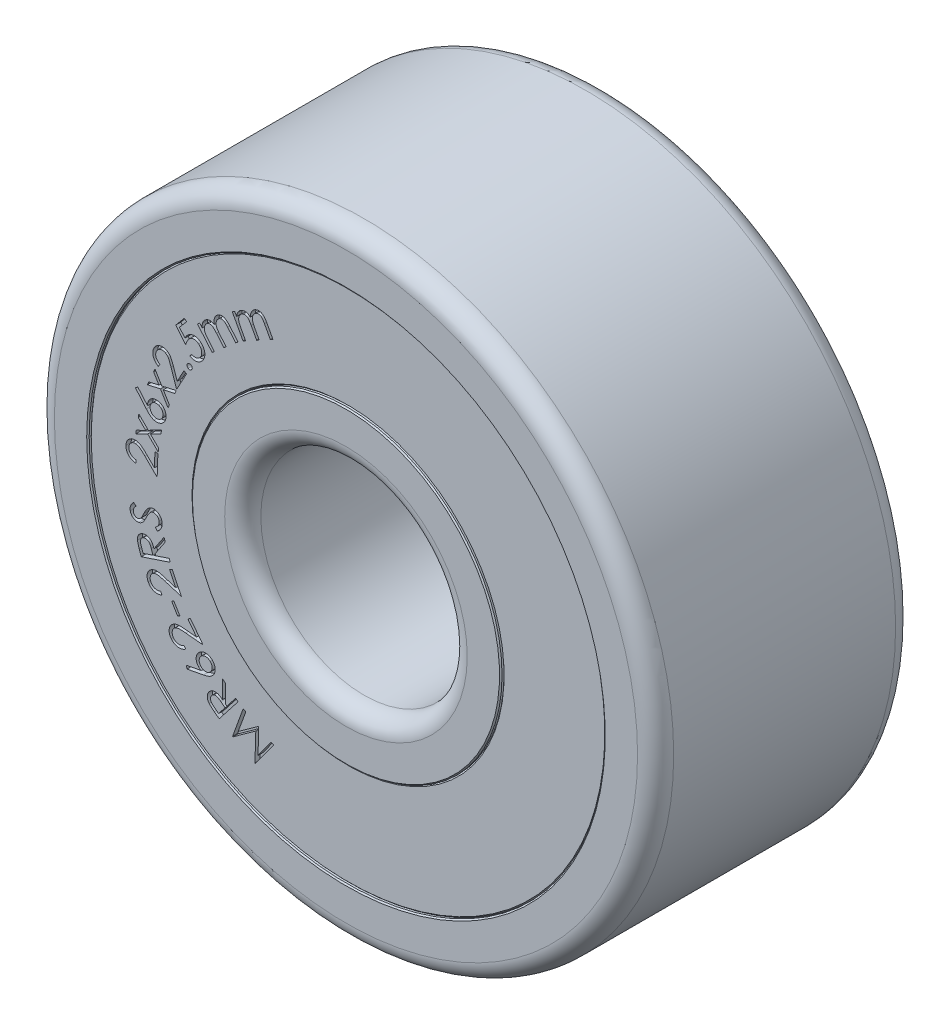
from build123d import *

# Parameters (mm, degrees)
SKETCH_R_INNER_BODY_W          = 2.5
SKETCH_R_INNER_BODY_H          = 0.5
FILLET_INNER_BODY_R            = 0.175
CHAMFER_INNER_BODY_SIZE        = 0.012
SKETCH_R_OUTER_BODY_W          = 2.5
SKETCH_R_OUTER_BODY_H          = 0.5
FILLET_OUTER_BODY_R            = 0.175
CHAMFER_OUTER_BODY_SIZE        = 0.012
SKETCH_R_SEAL_FACES_W          = 2.46
SKETCH_R_SEAL_FACES_H          = 1
CHAMFER_SEALS_SIZE             = 0.012
CUT_EXTRUDE_SEAL_LABEL_1_DEPTH = 0.05
CUT_EXTRUDE_SEAL_LABEL_2_DEPTH = 0.05


with BuildPart() as part:
    # Sketch R, INNER BODY → Revolve INNER BODY (revolve)
    with BuildSketch(Plane(origin=(0, 0, 0), x_dir=(0, 0, -1), z_dir=(1, 0, 0)), mode=Mode.PRIVATE) as revolve_inner_body_sk:
        with Locations((0, 1.25)):
            Rectangle(SKETCH_R_INNER_BODY_W, SKETCH_R_INNER_BODY_H)
    revolve(revolve_inner_body_sk.sketch.rotate(Axis((0, 0, 17.5), (0, 0, -1)), 90), axis=Axis((0, 0, 17.5), (0, 0, -1)))

    # Fillet INNER BODY
    fillet_inner_body_edges = [part.edges().sort_by_distance(p)[0] for p in [
        (-1, 0, -1.25),
        (-1, 0, 1.25),
    ]]
    fillet(fillet_inner_body_edges, radius=FILLET_INNER_BODY_R)

    # Chamfer INNER BODY
    chamfer_inner_body_edges = [part.edges().sort_by_distance(p)[0] for p in [
        (-1.5, 0, 1.25),
        (-1.5, 0, -1.25),
    ]]
    chamfer(chamfer_inner_body_edges, length=CHAMFER_INNER_BODY_SIZE)


with BuildPart() as body_2:
    # Sketch R, OUTER BODY → Revolve OUTER BODY (revolve)
    with BuildSketch(Plane(origin=(0, 0, 0), x_dir=(0, 0, -1), z_dir=(1, 0, 0)), mode=Mode.PRIVATE) as revolve_outer_body_sk:
        with Locations((0, 2.75)):
            Rectangle(SKETCH_R_OUTER_BODY_W, SKETCH_R_OUTER_BODY_H)
    revolve(revolve_outer_body_sk.sketch.rotate(Axis((0, 0, 17.5), (0, 0, -1)), 90), axis=Axis((0, 0, 17.5), (0, 0, -1)))

    # Fillet OUTER BODY
    fillet_outer_body_edges = [body_2.edges().sort_by_distance(p)[0] for p in [
        (-3, 0, 1.25),
        (-3, 0, -1.25),
    ]]
    fillet(fillet_outer_body_edges, radius=FILLET_OUTER_BODY_R)

    # Chamfer OUTER BODY
    chamfer_outer_body_edges = [body_2.edges().sort_by_distance(p)[0] for p in [
        (-2.5, 0, -1.25),
        (-2.5, 0, 1.25),
    ]]
    chamfer(chamfer_outer_body_edges, length=CHAMFER_OUTER_BODY_SIZE)


with BuildPart() as body_3:
    # Sketch R, SEAL FACES → Revolve SEALS (revolve)
    with BuildSketch(Plane(origin=(0, 0, 0), x_dir=(0, 0, -1), z_dir=(1, 0, 0)), mode=Mode.PRIVATE) as revolve_seals_sk:
        with Locations((0, 2)):
            Rectangle(SKETCH_R_SEAL_FACES_W, SKETCH_R_SEAL_FACES_H)
    revolve(revolve_seals_sk.sketch.rotate(Axis((0, 0, 17.5), (0, 0, -1)), 270), axis=Axis((0, 0, 17.5), (0, 0, -1)))

    # Chamfer SEALS
    chamfer_seals_edges = [body_3.edges().sort_by_distance(p)[0] for p in [
        (1.5, 0, -1.23),
        (1.5, 0, 1.23),
        (2.5, 0, 1.23),
        (2.5, 0, -1.23),
    ]]
    chamfer(chamfer_seals_edges, length=CHAMFER_SEALS_SIZE)

    # Sketch TEXT RADIUS 1 — MANUALLY ASSIGN TEXT AND FONT SIZE (FROM EQUATIONS) → Cut-Extrude SEAL LABEL 1 (cut)
    # profile 1 of 17: a face of its own
    with BuildSketch(Plane.XY.offset(1.23)):
        with BuildLine():
            Line((-1.122343833, 1.735663798), (-1.097524121, 1.749065241))
            Line((-1.097524121, 1.749065241), (-1.079375083, 1.715531587))
            add(Edge.make_bspline(
                [(-1.079375083, 1.715531587), (-1.078827205, 1.71961132), (-1.077777173, 1.727430306), (-1.075107246, 1.738470188), (-1.071777473, 1.74836696), (-1.068747296, 1.754283794), (-1.067295756, 1.757118125)],
                knots=[0, 0, 0, 0, 1.132946328, 2.171341033, 3.124020469, 4, 4, 4, 4], degree=3))
            add(Edge.make_bspline(
                [(-1.067295756, 1.757118125), (-1.065107574, 1.760574274), (-1.060790703, 1.767392606), (-1.052733974, 1.776281271), (-1.043798579, 1.784039802), (-1.037074458, 1.788043021), (-1.033702006, 1.790050818)],
                knots=[0, 0, 0, 0, 1.029422854, 2.03085757, 3.012385559, 4, 4, 4, 4], degree=3))
            add(Edge.make_bspline(
                [(-1.033702006, 1.790050818), (-1.031340527, 1.791241939), (-1.026657927, 1.793603824), (-1.019263361, 1.796265629), (-1.01167223, 1.798033547), (-1.00399064, 1.79912981), (-0.996374846, 1.799457345), (-0.989003562, 1.798894276), (-0.981962886, 1.79764768), (-0.975141843, 1.795578032), (-0.968371359, 1.792460062), (-0.961480778, 1.788256811), (-0.954261477, 1.782993477), (-0.949611077, 1.778836969), (-0.947163544, 1.776649375)],
                knots=[0, 0, 0, 0, 1.007893942, 1.99856265, 2.987934747, 3.975299643, 4.953789903, 5.888235043, 6.788718997, 7.675491184, 8.598470306, 9.622901381, 10.748919328, 12, 12, 12, 12], degree=3))
            add(Edge.make_bspline(
                [(-0.947163544, 1.776649375), (-0.947108468, 1.779074286), (-0.946999971, 1.78385121), (-0.946408092, 1.790899168), (-0.945364793, 1.797716081), (-0.944006561, 1.804303779), (-0.942251124, 1.810644495), (-0.940147292, 1.816756186), (-0.937635415, 1.822621421), (-0.933783857, 1.830046143), (-0.928247806, 1.838709305), (-0.92022596, 1.847825849), (-0.911138913, 1.855779517), (-0.904246357, 1.859864893), (-0.900769314, 1.861925818)],
                knots=[0, 0, 0, 0, 0.855519476, 1.685320073, 2.492825945, 3.286956377, 4.056723802, 4.812084644, 5.565525887, 6.305086716, 7.76143023, 9.178709332, 10.576761301, 12, 12, 12, 12], degree=3))
            add(Edge.make_bspline(
                [(-0.900769314, 1.861925818), (-0.897445438, 1.863568848), (-0.890929344, 1.866789829), (-0.880579018, 1.869840407), (-0.870157044, 1.871401842), (-0.859693621, 1.871256863), (-0.849426406, 1.869575766), (-0.83947686, 1.866388209), (-0.83009439, 1.861448084), (-0.822643565, 1.856194357), (-0.816883454, 1.851046148), (-0.812441047, 1.846454994), (-0.807906413, 1.841178216), (-0.803311922, 1.835200384), (-0.798700235, 1.828482592), (-0.793943841, 1.8211328), (-0.789058521, 1.813106739), (-0.785961353, 1.807412434), (-0.784363064, 1.804473894)],
                knots=[0, 0, 0, 0, 1.202692996, 2.35774762, 3.488867218, 4.614807807, 5.742477376, 6.857930864, 7.993087118, 9.174031987, 9.810143083, 10.500470647, 11.248000588, 12.069362592, 12.94853042, 13.894416233, 14.913415839, 16, 16, 16, 16], degree=3))
            Line((-0.784363064, 1.804473894), (-0.727091429, 1.698524375))
            Line((-0.727091429, 1.698524375), (-0.752572198, 1.68470226))
            Line((-0.752572198, 1.68470226), (-0.809843833, 1.790651779))
            add(Edge.make_bspline(
                [(-0.809843833, 1.790651779), (-0.811213851, 1.793142663), (-0.81384728, 1.797930603), (-0.817827411, 1.80470367), (-0.821525921, 1.810844247), (-0.825052931, 1.816286172), (-0.828493714, 1.820961928), (-0.831677202, 1.824992338), (-0.834583692, 1.828425335), (-0.838342709, 1.831909729), (-0.843125893, 1.835411424), (-0.849266004, 1.838706379), (-0.855983287, 1.840767008), (-0.863060733, 1.841922861), (-0.870402198, 1.841985839), (-0.877855358, 1.840863827), (-0.885368684, 1.838587931), (-0.890144048, 1.836179429), (-0.892596237, 1.834942644)],
                knots=[0, 0, 0, 0, 1.262703955, 2.427150203, 3.489288599, 4.446873273, 5.306509657, 6.066671534, 6.728798716, 7.30168236, 8.339272186, 9.354217877, 10.381377087, 11.444893699, 12.530515548, 13.627853015, 14.781883155, 16, 16, 16, 16], degree=3))
            add(Edge.make_bspline(
                [(-0.892596237, 1.834942644), (-0.89550428, 1.83321028), (-0.901270405, 1.829775314), (-0.908783135, 1.823032611), (-0.915167643, 1.815171534), (-0.920333026, 1.806319478), (-0.924274227, 1.796764722), (-0.926690006, 1.786706923), (-0.927573016, 1.776302115), (-0.927107949, 1.767353359), (-0.925734122, 1.759812556), (-0.924073252, 1.753477659), (-0.921824658, 1.746505366), (-0.919006656, 1.738874064), (-0.915489078, 1.730654757), (-0.911375529, 1.721809651), (-0.906712599, 1.712307355), (-0.903235142, 1.705844755), (-0.901430371, 1.702490721)],
                knots=[0, 0, 0, 0, 1.078086967, 2.137651911, 3.200874055, 4.29826911, 5.396278353, 6.487755879, 7.585020608, 8.718245508, 9.335151436, 10.028168088, 10.806470145, 11.672089206, 12.623068298, 13.658388782, 14.784723943, 16, 16, 16, 16], degree=3))
            Line((-0.901430371, 1.702490721), (-0.860324602, 1.626469087))
            Line((-0.860324602, 1.626469087), (-0.885144314, 1.613007548))
            Line((-0.885144314, 1.613007548), (-0.938870275, 1.712406587))
            add(Edge.make_bspline(
                [(-0.938870275, 1.712406587), (-0.940398896, 1.715218788), (-0.94332068, 1.720593991), (-0.947735329, 1.728193134), (-0.951875993, 1.735016275), (-0.955674657, 1.741126952), (-0.959373405, 1.746367218), (-0.962778563, 1.750857854), (-0.965878903, 1.75465535), (-0.969779621, 1.758526368), (-0.974680866, 1.762485511), (-0.981108534, 1.765999271), (-0.987972448, 1.768507379), (-0.995237517, 1.769862166), (-1.002746073, 1.770139681), (-1.010307646, 1.769067114), (-1.017891796, 1.766825359), (-1.022694942, 1.764463954), (-1.025168352, 1.763247933)],
                knots=[0, 0, 0, 0, 1.336305489, 2.554195278, 3.66867879, 4.668704831, 5.557365218, 6.345224332, 7.021997584, 7.601559619, 8.637353205, 9.640591628, 10.645954342, 11.676059688, 12.713675014, 13.768738341, 14.85099789, 16, 16, 16, 16], degree=3))
            add(Edge.make_bspline(
                [(-1.025168352, 1.763247933), (-1.027953183, 1.7615707), (-1.033477746, 1.758243397), (-1.040724583, 1.751708817), (-1.046949333, 1.744049505), (-1.05215196, 1.735376663), (-1.056087948, 1.725940324), (-1.058666024, 1.715986928), (-1.059741631, 1.705658767), (-1.059362205, 1.696761182), (-1.058286686, 1.689317827), (-1.05676718, 1.683239219), (-1.054865298, 1.67668878), (-1.052365719, 1.669671034), (-1.049284878, 1.662215847), (-1.045742692, 1.654237719), (-1.041581069, 1.645865336), (-1.03856271, 1.640164198), (-1.037007294, 1.637226298)],
                knots=[0, 0, 0, 0, 1.089941684, 2.162232425, 3.25725062, 4.39503195, 5.547166843, 6.679743556, 7.836682095, 9.021842795, 9.661302689, 10.359808926, 11.124173149, 11.952003323, 12.860382206, 13.833233437, 14.883425913, 16, 16, 16, 16], degree=3))
            Line((-1.037007294, 1.637226298), (-0.99253614, 1.554954664))
            Line((-0.99253614, 1.554954664), (-1.017355852, 1.541553221))
            Line((-1.017355852, 1.541553221), (-1.122343833, 1.735663798))
        make_face()
    # profile 2 of 17: a face of its own
    with BuildSketch(Plane.XY.offset(1.23)):
        with BuildLine():
            Line((-1.459018351, 1.463078499), (-1.43762412, 1.481287633))
            Line((-1.43762412, 1.481287633), (-1.412924601, 1.452321287))
            add(Edge.make_bspline(
                [(-1.412924601, 1.452321287), (-1.413242985, 1.456425955), (-1.413851405, 1.464269818), (-1.413497272, 1.4755874), (-1.412412764, 1.485948354), (-1.410606181, 1.492342669), (-1.409739504, 1.49541023)],
                knots=[0, 0, 0, 0, 1.135219144, 2.169360364, 3.121782839, 4, 4, 4, 4], degree=3))
            add(Edge.make_bspline(
                [(-1.409739504, 1.49541023), (-1.408323331, 1.499244208), (-1.405540428, 1.50677831), (-1.399575012, 1.51715029), (-1.39244352, 1.526531814), (-1.38670579, 1.531826457), (-1.383838062, 1.53447273)],
                knots=[0, 0, 0, 0, 1.032230273, 2.028422137, 3.014601769, 4, 4, 4, 4], degree=3))
            add(Edge.make_bspline(
                [(-1.383838062, 1.53447273), (-1.381786245, 1.536118195), (-1.377690612, 1.53940271), (-1.371041474, 1.543523454), (-1.364013445, 1.54686312), (-1.356749604, 1.549497483), (-1.349371717, 1.551314165), (-1.342092162, 1.552483294), (-1.334968582, 1.552617771), (-1.32787603, 1.552056347), (-1.320624345, 1.550390714), (-1.312985732, 1.547794286), (-1.304893548, 1.544056053), (-1.299481302, 1.541003798), (-1.296638543, 1.539400614)],
                knots=[0, 0, 0, 0, 1.004964279, 2.006009869, 2.982372572, 3.975711588, 4.954684449, 5.884073181, 6.788153086, 7.672287117, 8.597754093, 9.624718013, 10.752393362, 12, 12, 12, 12], degree=3))
            add(Edge.make_bspline(
                [(-1.296638543, 1.539400614), (-1.297078972, 1.541780876), (-1.297945715, 1.54646511), (-1.298888962, 1.553460231), (-1.299260427, 1.560307991), (-1.299385026, 1.566992027), (-1.298907708, 1.573510695), (-1.29818108, 1.57990708), (-1.296878186, 1.586138287), (-1.294756222, 1.594208358), (-1.291063449, 1.603770796), (-1.285150584, 1.614343042), (-1.277958231, 1.62399674), (-1.272070877, 1.62941045), (-1.269114504, 1.63212898)],
                knots=[0, 0, 0, 0, 0.856914002, 1.686363576, 2.496304063, 3.283479745, 4.050956338, 4.808275092, 5.560664027, 6.302044508, 7.76121653, 9.173898035, 10.580854563, 12, 12, 12, 12], degree=3))
            add(Edge.make_bspline(
                [(-1.269114504, 1.63212898), (-1.266191255, 1.634441028), (-1.260486736, 1.638952828), (-1.251015934, 1.644127469), (-1.241137682, 1.647693008), (-1.230929859, 1.649760855), (-1.220574682, 1.650235754), (-1.210230243, 1.649160019), (-1.200025613, 1.646388222), (-1.191697987, 1.642769185), (-1.185023697, 1.638946725), (-1.17973775, 1.635372327), (-1.174215796, 1.631164643), (-1.168508816, 1.626278237), (-1.162598356, 1.620698722), (-1.156454812, 1.614476372), (-1.150059309, 1.607621471), (-1.145859991, 1.602737335), (-1.143693831, 1.600217922)],
                knots=[0, 0, 0, 0, 1.212522353, 2.366153014, 3.497417146, 4.622395747, 5.746067543, 6.861675515, 7.99667925, 9.177492225, 9.808856064, 10.500264946, 11.254679421, 12.069400805, 12.946597164, 13.901814498, 14.917680461, 16, 16, 16, 16], degree=3))
            Line((-1.143693831, 1.600217922), (-1.065869312, 1.508751576))
            Line((-1.065869312, 1.508751576), (-1.087864504, 1.490001576))
            Line((-1.087864504, 1.490001576), (-1.165689024, 1.581467922))
            add(Edge.make_bspline(
                [(-1.165689024, 1.581467922), (-1.167546693, 1.583615919), (-1.171111761, 1.58773816), (-1.176318226, 1.593588308), (-1.181242995, 1.598745236), (-1.185822484, 1.603285202), (-1.190085078, 1.607203918), (-1.194024628, 1.610507163), (-1.197619914, 1.613187874), (-1.201953109, 1.615829891), (-1.207293041, 1.61831515), (-1.214014325, 1.620041611), (-1.220983019, 1.62078019), (-1.228134978, 1.620395339), (-1.23531933, 1.618965963), (-1.242373035, 1.616329098), (-1.249226566, 1.612520854), (-1.253393988, 1.609195949), (-1.255532774, 1.607489557)],
                knots=[0, 0, 0, 0, 1.265496125, 2.428624534, 3.489346951, 4.442485142, 5.301756917, 6.06866268, 6.73283755, 7.29775587, 8.328339365, 9.343812217, 10.375940931, 11.439551612, 12.523201375, 13.627536957, 14.782415149, 16, 16, 16, 16], degree=3))
            add(Edge.make_bspline(
                [(-1.255532774, 1.607489557), (-1.258020431, 1.605203497), (-1.262950051, 1.60067337), (-1.268848476, 1.592525451), (-1.273491315, 1.583580404), (-1.276688368, 1.573876466), (-1.278490533, 1.563738516), (-1.278825246, 1.553423333), (-1.277481817, 1.543092305), (-1.275226381, 1.534443781), (-1.272315423, 1.527352752), (-1.26942832, 1.521489363), (-1.265792915, 1.515148823), (-1.261351577, 1.508390875), (-1.256325018, 1.501031549), (-1.250490365, 1.493233099), (-1.24383575, 1.485022892), (-1.239153208, 1.47939906), (-1.236722677, 1.476479941)],
                knots=[0, 0, 0, 0, 1.078798937, 2.137781611, 3.198547607, 4.293151471, 5.393390277, 6.483574521, 7.581570305, 8.716660756, 9.332061491, 10.031553294, 10.806748636, 11.669088591, 12.618559207, 13.658276787, 14.784500059, 16, 16, 16, 16], degree=3))
            Line((-1.236722677, 1.476479941), (-1.180893351, 1.410854941))
            Line((-1.180893351, 1.410854941), (-1.202287581, 1.392645807))
            Line((-1.202287581, 1.392645807), (-1.275244312, 1.478403018))
            add(Edge.make_bspline(
                [(-1.275244312, 1.478403018), (-1.277318416, 1.480814944), (-1.281307041, 1.485453221), (-1.287179882, 1.491982992), (-1.292640618, 1.497822889), (-1.297686447, 1.50293701), (-1.302306913, 1.507360378), (-1.306563966, 1.511025872), (-1.310424305, 1.514014682), (-1.314982856, 1.517026643), (-1.320606231, 1.519785414), (-1.327565444, 1.521913434), (-1.334764576, 1.522970419), (-1.342127288, 1.52274523), (-1.34948572, 1.521457703), (-1.356636245, 1.51885241), (-1.363619997, 1.51518545), (-1.367802537, 1.511850654), (-1.369955851, 1.510133787)],
                knots=[0, 0, 0, 0, 1.332118097, 2.561742036, 3.677496279, 4.67999526, 5.570087988, 6.355334932, 7.031512975, 7.613196629, 8.641169753, 9.641560575, 10.64997385, 11.673728118, 12.713680146, 13.764403586, 14.849039054, 16, 16, 16, 16], degree=3))
            add(Edge.make_bspline(
                [(-1.369955851, 1.510133787), (-1.372309528, 1.50791606), (-1.376990335, 1.503505617), (-1.382795087, 1.495676461), (-1.38720133, 1.486857723), (-1.390518405, 1.477352058), (-1.392433191, 1.467332837), (-1.392890399, 1.457098631), (-1.391657248, 1.446810626), (-1.389538786, 1.438218742), (-1.386904741, 1.431193257), (-1.384218272, 1.425557099), (-1.380975345, 1.419556038), (-1.377101575, 1.413218877), (-1.372568931, 1.406571653), (-1.367476573, 1.39952742), (-1.361676532, 1.392208474), (-1.357547456, 1.387267677), (-1.355412581, 1.384713114)],
                knots=[0, 0, 0, 0, 1.087658858, 2.163050455, 3.261307462, 4.39634991, 5.543497851, 6.684619069, 7.831945538, 9.021496939, 9.655551991, 10.355750247, 11.122470385, 11.952059621, 12.855827046, 13.831471104, 14.878795869, 16, 16, 16, 16], degree=3))
            Line((-1.355412581, 1.384713114), (-1.295015947, 1.313739557))
            Line((-1.295015947, 1.313739557), (-1.316410177, 1.295530422))
            Line((-1.316410177, 1.295530422), (-1.459018351, 1.463078499))
        make_face()
    # profile 3 of 17: a face of its own
    with BuildSketch(Plane.XY.offset(1.23)):
        with BuildLine():
            Line((-1.586053844, 1.44789017), (-1.56423894, 1.429620939))
            Line((-1.56423894, 1.429620939), (-1.632808652, 1.347950266))
            Line((-1.632808652, 1.347950266), (-1.57986394, 1.284068055))
            add(Edge.make_bspline(
                [(-1.57986394, 1.284068055), (-1.578497786, 1.28705059), (-1.575846986, 1.292837713), (-1.571410639, 1.300940665), (-1.566731413, 1.308233014), (-1.563272449, 1.312599277), (-1.561594709, 1.314717093)],
                knots=[0, 0, 0, 0, 1.099524704, 2.13344848, 3.094645842, 4, 4, 4, 4], degree=3))
            add(Edge.make_bspline(
                [(-1.561594709, 1.314717093), (-1.559373845, 1.317221674), (-1.555026048, 1.322124905), (-1.54788079, 1.328674491), (-1.540326242, 1.33427202), (-1.532465926, 1.339063663), (-1.524185532, 1.342865885), (-1.515583233, 1.345854828), (-1.506558369, 1.347792645), (-1.497286916, 1.348965317), (-1.487904172, 1.349112507), (-1.478596552, 1.348428076), (-1.469466846, 1.346694108), (-1.460458868, 1.344143479), (-1.451673448, 1.340471339), (-1.443031899, 1.335951392), (-1.434581781, 1.330448336), (-1.429229772, 1.326199995), (-1.426498555, 1.324031997)],
                knots=[0, 0, 0, 0, 1.057951054, 2.071155792, 3.05800254, 4.026961825, 4.976324716, 5.933788031, 6.900425856, 7.889546635, 8.884168414, 9.862563495, 10.835303957, 11.817586851, 12.817398522, 13.840180039, 14.897808706, 16, 16, 16, 16], degree=3))
            add(Edge.make_bspline(
                [(-1.426498555, 1.324031997), (-1.424655042, 1.322431719), (-1.421013923, 1.319271012), (-1.415952224, 1.314176836), (-1.41124442, 1.308904913), (-1.406978394, 1.303341112), (-1.403049693, 1.297582398), (-1.39957092, 1.291539231), (-1.396440442, 1.285306781), (-1.392864913, 1.276791355), (-1.38948571, 1.265944669), (-1.387084177, 1.252717944), (-1.386849576, 1.239433901), (-1.388094947, 1.228432315), (-1.389998682, 1.21974279), (-1.391937006, 1.21327774), (-1.394352528, 1.206924314), (-1.397166585, 1.200643058), (-1.400512936, 1.194509452), (-1.40424233, 1.188417686), (-1.408432123, 1.182396098), (-1.411568711, 1.178559264), (-1.413157209, 1.176616132)],
                knots=[0, 0, 0, 0, 0.88285087, 1.7437166, 2.595875965, 3.438023981, 4.278174163, 5.115914388, 5.958529961, 6.799710869, 8.454565936, 10.05817063, 11.645614618, 13.242952196, 14.05176472, 14.861096505, 15.682120765, 16.509167405, 17.348942464, 18.207762183, 19.092336386, 20, 20, 20, 20], degree=3))
            add(Edge.make_bspline(
                [(-1.413157209, 1.176616132), (-1.415123015, 1.174377083), (-1.418988076, 1.169974787), (-1.425340427, 1.164078246), (-1.431965532, 1.158877705), (-1.438902402, 1.154400086), (-1.446162275, 1.15067622), (-1.453696454, 1.147552331), (-1.461589142, 1.145303851), (-1.469694271, 1.143745944), (-1.477899351, 1.142889436), (-1.486087531, 1.142843402), (-1.494192635, 1.143503455), (-1.502196921, 1.144891694), (-1.510130643, 1.146998896), (-1.517936825, 1.149915998), (-1.525700351, 1.153513131), (-1.530650251, 1.15647768), (-1.533169228, 1.157986324)],
                knots=[0, 0, 0, 0, 1.072496443, 2.108685047, 3.116016703, 4.10259632, 5.077046759, 6.05101637, 7.035060468, 8.026901601, 9.020420533, 10.001604339, 10.971584614, 11.945340448, 12.923575796, 13.923335371, 14.943196254, 16, 16, 16, 16], degree=3))
            Line((-1.533169228, 1.157986324), (-1.513397594, 1.181544016))
            add(Edge.make_bspline(
                [(-1.513397594, 1.181544016), (-1.510876049, 1.180254464), (-1.506028183, 1.177775199), (-1.498632594, 1.174943536), (-1.491456285, 1.173214662), (-1.484478956, 1.172299291), (-1.47757972, 1.172440108), (-1.470696782, 1.173516253), (-1.463741621, 1.175294068), (-1.456868772, 1.178031295), (-1.45022691, 1.181447115), (-1.444009427, 1.185586967), (-1.438334489, 1.190385541), (-1.435012787, 1.194064726), (-1.433349517, 1.195906997)],
                knots=[0, 0, 0, 0, 1.149293788, 2.209606258, 3.205662792, 4.139701188, 5.058786582, 5.996111554, 6.962615511, 7.966871268, 8.992563814, 9.989483109, 10.99327779, 12, 12, 12, 12], degree=3))
            add(Edge.make_bspline(
                [(-1.433349517, 1.195906997), (-1.43185086, 1.197803257), (-1.428890105, 1.201549519), (-1.42512154, 1.207584334), (-1.422204951, 1.213931847), (-1.419886092, 1.220483756), (-1.418233407, 1.227284589), (-1.41743808, 1.234366281), (-1.417242395, 1.241668138), (-1.417790094, 1.249135445), (-1.419051057, 1.256595842), (-1.420952385, 1.2638695), (-1.423583552, 1.270868684), (-1.426857062, 1.27760086), (-1.430957042, 1.283996471), (-1.435645307, 1.2901586), (-1.441069907, 1.296006356), (-1.445116167, 1.299566981), (-1.447171632, 1.301375747)],
                knots=[0, 0, 0, 0, 0.978912495, 1.933944233, 2.874447548, 3.803746025, 4.7467678, 5.70321269, 6.685652204, 7.702883716, 8.731707251, 9.747610172, 10.744165154, 11.756950405, 12.774797019, 13.817044847, 14.891077983, 16, 16, 16, 16], degree=3))
            add(Edge.make_bspline(
                [(-1.447171632, 1.301375747), (-1.449087453, 1.302915256), (-1.452858366, 1.305945475), (-1.458870722, 1.309767778), (-1.464983868, 1.312932551), (-1.471203665, 1.315407638), (-1.477537934, 1.317245497), (-1.48401311, 1.318307478), (-1.490597569, 1.31875252), (-1.497243072, 1.318425923), (-1.50382944, 1.317483537), (-1.510282758, 1.315847709), (-1.516519546, 1.313490561), (-1.522584372, 1.310484888), (-1.528369527, 1.30667936), (-1.534044512, 1.302311786), (-1.539463087, 1.297163563), (-1.542813891, 1.29334996), (-1.544527402, 1.291399786)],
                knots=[0, 0, 0, 0, 1.069743425, 2.105577751, 3.096686608, 4.063891077, 5.01662482, 5.96326716, 6.916200617, 7.885606139, 8.855404181, 9.809734462, 10.778786581, 11.754219391, 12.751262512, 13.78962895, 14.8696758, 16, 16, 16, 16], degree=3))
            add(Edge.make_bspline(
                [(-1.544527402, 1.291399786), (-1.545933383, 1.289634715), (-1.548831822, 1.285996013), (-1.552840299, 1.28002602), (-1.556676852, 1.273444901), (-1.560391034, 1.266307165), (-1.563959154, 1.258573493), (-1.567287377, 1.250235841), (-1.570484054, 1.241311933), (-1.572432721, 1.235136627), (-1.573433652, 1.231964689)],
                knots=[0, 0, 0, 0, 0.814004859, 1.678075476, 2.591727332, 3.561633421, 4.580406376, 5.663607227, 6.799914686, 8, 8, 8, 8], degree=3))
            Line((-1.573433652, 1.231964689), (-1.669347113, 1.348611324))
            Line((-1.669347113, 1.348611324), (-1.586053844, 1.44789017))
        make_face()
    # profile 4 of 17: a face of its own
    with BuildSketch(Plane.XY.offset(1.23)):
        with BuildLine():
            add(Edge.make_bspline(
                [(-1.555069803, 1.080873724), (-1.554063611, 1.082208773), (-1.552083513, 1.084836033), (-1.548173335, 1.087832419), (-1.54384971, 1.090149209), (-1.53903966, 1.091407526), (-1.534090615, 1.091860467), (-1.529190544, 1.091301052), (-1.524431837, 1.08980441), (-1.521603362, 1.088031986), (-1.520153937, 1.087123724)],
                knots=[0, 0, 0, 0, 1.012747625, 1.993000145, 2.968772268, 3.979978698, 4.995143473, 5.976304756, 6.962976316, 8, 8, 8, 8], degree=3))
            add(Edge.make_bspline(
                [(-1.520153937, 1.087123724), (-1.518825256, 1.086112957), (-1.516200525, 1.084116246), (-1.513113569, 1.080265818), (-1.51089687, 1.07585699), (-1.509559618, 1.071061089), (-1.509050492, 1.06608992), (-1.509537537, 1.061208469), (-1.510981051, 1.056488296), (-1.512715081, 1.053697653), (-1.513603456, 1.052267955)],
                knots=[0, 0, 0, 0, 1.014656579, 2.004393836, 2.976422535, 4.004581701, 5.022758857, 6.004479466, 6.977657905, 8, 8, 8, 8], degree=3))
            add(Edge.make_bspline(
                [(-1.513603456, 1.052267955), (-1.514635991, 1.050940461), (-1.516650647, 1.048350287), (-1.520496611, 1.045258696), (-1.524908794, 1.043073645), (-1.52973168, 1.041793402), (-1.534702788, 1.041344171), (-1.539586608, 1.041889979), (-1.544287939, 1.043407678), (-1.547087661, 1.045134785), (-1.548519322, 1.046017955)],
                knots=[0, 0, 0, 0, 1.022202317, 1.994496069, 2.977156368, 4.001761216, 5.018555404, 6.001291523, 6.977943472, 8, 8, 8, 8], degree=3))
            add(Edge.make_bspline(
                [(-1.548519322, 1.046017955), (-1.549869379, 1.047047625), (-1.552514395, 1.049064941), (-1.555630141, 1.052961238), (-1.557877279, 1.057359502), (-1.559262765, 1.062155691), (-1.559657074, 1.067094372), (-1.559212992, 1.071964131), (-1.557674248, 1.07664183), (-1.555951, 1.07944189), (-1.555069803, 1.080873724)],
                knots=[0, 0, 0, 0, 1.030256292, 2.01846447, 3.005393316, 4.020241408, 5.035748373, 6.003821812, 6.979237357, 8, 8, 8, 8], degree=3))
        make_face()
    # profile 5 of 17: a face of its own
    with BuildSketch(Plane.XY.offset(1.23)):
        with BuildLine():
            Line((-1.824070779, 0.94269035), (-1.837712605, 0.917510062))
            add(Edge.make_bspline(
                [(-1.837712605, 0.917510062), (-1.840815464, 0.919396846), (-1.846888385, 0.923089664), (-1.855203991, 0.929492383), (-1.862783234, 0.936247438), (-1.869427717, 0.943656038), (-1.875252616, 0.951528337), (-1.880317714, 0.95986525), (-1.884388683, 0.968782639), (-1.887675331, 0.978092623), (-1.890081316, 0.987626739), (-1.891466718, 0.997212078), (-1.891924936, 1.006718738), (-1.891266817, 1.016175923), (-1.88980475, 1.025592422), (-1.887230436, 1.034919656), (-1.883750491, 1.044218207), (-1.880683452, 1.050170644), (-1.879118855, 1.053207177)],
                knots=[0, 0, 0, 0, 1.101924003, 2.156687473, 3.181652098, 4.180843647, 5.172340557, 6.151880089, 7.137069119, 8.14321643, 9.146399144, 10.117593301, 11.079600848, 12.03044786, 12.99145492, 13.968271087, 14.963548405, 16, 16, 16, 16], degree=3))
            add(Edge.make_bspline(
                [(-1.879118855, 1.053207177), (-1.877452265, 1.056127411), (-1.874199676, 1.061826662), (-1.868467603, 1.069616242), (-1.862327985, 1.076648475), (-1.855665646, 1.082866226), (-1.848438419, 1.088179355), (-1.840782364, 1.092720416), (-1.832603624, 1.096424421), (-1.823992748, 1.099167655), (-1.815236263, 1.101244695), (-1.806474898, 1.102350093), (-1.797843729, 1.102777192), (-1.789334108, 1.102178844), (-1.780922142, 1.100907175), (-1.772678192, 1.098607889), (-1.764482757, 1.095657726), (-1.759280365, 1.092970812), (-1.756642894, 1.091608619)],
                knots=[0, 0, 0, 0, 1.125434309, 2.196445452, 3.232911465, 4.248977359, 5.242073912, 6.231741639, 7.225767157, 8.242165333, 9.254568916, 10.235830117, 11.196198448, 12.144227991, 13.088522077, 14.04072172, 15.006699453, 16, 16, 16, 16], degree=3))
            add(Edge.make_bspline(
                [(-1.756642894, 1.091608619), (-1.753035248, 1.089476669), (-1.745905479, 1.085263309), (-1.736320372, 1.077349969), (-1.727791783, 1.068357005), (-1.721578764, 1.059821002), (-1.716980354, 1.052175917), (-1.713440012, 1.045522711), (-1.709799222, 1.038013918), (-1.706012191, 1.029666087), (-1.702160751, 1.02044871), (-1.698294571, 1.010346903), (-1.694233094, 0.999407322), (-1.691639935, 0.991775607), (-1.69029674, 0.987822562)],
                knots=[0, 0, 0, 0, 1.192008222, 2.355758747, 3.526161442, 4.714107456, 5.354030055, 6.066201884, 6.859767274, 7.730473944, 8.676695749, 9.704446459, 10.810958423, 12, 12, 12, 12], degree=3))
            Line((-1.69029674, 0.987822562), (-1.655320779, 0.884276889))
            Line((-1.655320779, 0.884276889), (-1.58951549, 1.005430735))
            Line((-1.58951549, 1.005430735), (-1.564154913, 0.991668715))
            Line((-1.564154913, 0.991668715), (-1.660969817, 0.813423523))
            Line((-1.660969817, 0.813423523), (-1.714815971, 0.972498042))
            add(Edge.make_bspline(
                [(-1.714815971, 0.972498042), (-1.716100888, 0.976370134), (-1.718565254, 0.983796494), (-1.72238645, 0.994395818), (-1.725989955, 1.004072586), (-1.729364272, 1.012837465), (-1.732685081, 1.020599155), (-1.735809693, 1.02741357), (-1.738728654, 1.033301069), (-1.742349719, 1.039843935), (-1.747306054, 1.046901904), (-1.75396243, 1.054334534), (-1.76152119, 1.060734741), (-1.76714785, 1.064080621), (-1.76998424, 1.065767273)],
                knots=[0, 0, 0, 0, 1.321780634, 2.535068755, 3.65022817, 4.667483109, 5.577667619, 6.385011738, 7.096147476, 7.706383098, 8.80650101, 9.881833079, 10.932235596, 12, 12, 12, 12], degree=3))
            add(Edge.make_bspline(
                [(-1.76998424, 1.065767273), (-1.771828386, 1.066710877), (-1.775456791, 1.068567441), (-1.781176726, 1.070599788), (-1.786952602, 1.072054519), (-1.792812888, 1.072894759), (-1.798755728, 1.0731578), (-1.804793553, 1.072698006), (-1.810938816, 1.071692925), (-1.817065722, 1.070000379), (-1.823056535, 1.067786521), (-1.828762647, 1.065098606), (-1.834106584, 1.061913149), (-1.83898741, 1.058119864), (-1.843594138, 1.053916667), (-1.84779023, 1.049154354), (-1.851609222, 1.043897306), (-1.853791898, 1.040107389), (-1.854900105, 1.038183139)],
                knots=[0, 0, 0, 0, 1.000471395, 1.968453413, 2.926698893, 3.875750352, 4.825542583, 5.796281632, 6.797643064, 7.831261211, 8.863790097, 9.88173018, 10.876514763, 11.864299062, 12.864864183, 13.88698719, 14.927162029, 16, 16, 16, 16], degree=3))
            add(Edge.make_bspline(
                [(-1.854900105, 1.038183139), (-1.855954529, 1.036095296), (-1.858027159, 1.031991326), (-1.860530365, 1.025655657), (-1.86225331, 1.019279966), (-1.863372267, 1.012882735), (-1.863776886, 1.006477546), (-1.863562129, 1.000026745), (-1.862543788, 0.993598422), (-1.861030302, 0.987153734), (-1.858711716, 0.980842158), (-1.855771915, 0.974692497), (-1.852119472, 0.968772517), (-1.84784751, 0.963050194), (-1.842886389, 0.957572117), (-1.837267142, 0.952315168), (-1.830935853, 0.947346388), (-1.82639366, 0.944265777), (-1.824070779, 0.94269035)],
                knots=[0, 0, 0, 0, 1.004351244, 1.974204114, 2.919746415, 3.836347205, 4.75894536, 5.671620648, 6.602486585, 7.54990605, 8.510671201, 9.48429509, 10.472971535, 11.493409801, 12.547358397, 13.64307963, 14.794669178, 16, 16, 16, 16], degree=3))
        make_face()
    # profile 6 of 17: a face of its own
    with BuildSketch(Plane.XY.offset(1.23)):
        Polygon((-1.943430801, 0.711070508), (-1.929969263, 0.742320508), (-1.831952436, 0.763594546), (-1.883875513, 0.849411854), (-1.870413974, 0.880661854), (-1.804067821, 0.770084931), (-1.664344263, 0.802236373), (-1.67798609, 0.770625796), (-1.789584648, 0.745325316), (-1.730930801, 0.647729162), (-1.744272148, 0.61665945), (-1.817469263, 0.73901522), align=None)
    # profile 7 of 17: a face of its own
    with BuildSketch(Plane.XY.offset(1.23)):
        with BuildLine():
            Line((-2.059708139, 0.627180527), (-2.037532659, 0.6463512))
            Line((-2.037532659, 0.6463512), (-1.942099966, 0.535353604))
            add(Edge.make_bspline(
                [(-1.942099966, 0.535353604), (-1.942186686, 0.538138795), (-1.942355901, 0.543573493), (-1.941824372, 0.551503526), (-1.940898273, 0.559028462), (-1.939647887, 0.56378944), (-1.939035063, 0.566122835)],
                knots=[0, 0, 0, 0, 1.076128775, 2.099833165, 3.068712499, 4, 4, 4, 4], degree=3))
            add(Edge.make_bspline(
                [(-1.939035063, 0.566122835), (-1.938177546, 0.568911361), (-1.936491618, 0.57439377), (-1.93289325, 0.582105907), (-1.928858256, 0.589408857), (-1.923946647, 0.596048249), (-1.91844654, 0.602206522), (-1.912191564, 0.607725467), (-1.905346762, 0.612808322), (-1.897846717, 0.617199778), (-1.889981414, 0.620978898), (-1.881856358, 0.623954625), (-1.873545965, 0.625976861), (-1.865121714, 0.627289707), (-1.856540585, 0.627597107), (-1.847827346, 0.627202958), (-1.838968795, 0.625876964), (-1.833113547, 0.624349999), (-1.830140832, 0.623574758)],
                knots=[0, 0, 0, 0, 1.019429855, 2.004259415, 2.970867526, 3.933861375, 4.886600499, 5.854452652, 6.846833478, 7.864841113, 8.889868247, 9.89635259, 10.885585786, 11.877694377, 12.873730757, 13.884087004, 14.925749103, 16, 16, 16, 16], degree=3))
            add(Edge.make_bspline(
                [(-1.830140832, 0.623574758), (-1.82613397, 0.622297046), (-1.818264281, 0.619787553), (-1.807279645, 0.61426791), (-1.797288217, 0.607531886), (-1.788438808, 0.599473797), (-1.780708317, 0.590416591), (-1.774362459, 0.580319711), (-1.769294205, 0.569350729), (-1.76585316, 0.557553928), (-1.763693678, 0.545355587), (-1.763258309, 0.532995193), (-1.764247281, 0.520627304), (-1.766264156, 0.512596583), (-1.767280255, 0.508550719)],
                knots=[0, 0, 0, 0, 1.034394087, 2.031604916, 3.015400402, 3.993352797, 4.969898146, 5.938888002, 6.921210489, 7.935708811, 8.956794737, 9.963949813, 10.974241323, 12, 12, 12, 12], degree=3))
            add(Edge.make_bspline(
                [(-1.767280255, 0.508550719), (-1.768521362, 0.504705013), (-1.770969158, 0.497120249), (-1.776396092, 0.486462879), (-1.783073642, 0.476643552), (-1.791008572, 0.467745199), (-1.800011707, 0.459993432), (-1.809954122, 0.453525629), (-1.820812211, 0.448609203), (-1.832323204, 0.445072158), (-1.84422349, 0.443035475), (-1.856238017, 0.442554213), (-1.868233614, 0.443590834), (-1.876033247, 0.445506706), (-1.879960543, 0.446471392)],
                knots=[0, 0, 0, 0, 1.013998636, 1.999877226, 2.992426707, 3.99054985, 4.986297187, 5.969126243, 6.960079317, 7.971025542, 8.987120508, 9.984481977, 10.985139847, 12, 12, 12, 12], degree=3))
            add(Edge.make_bspline(
                [(-1.879960543, 0.446471392), (-1.882907642, 0.447413859), (-1.88891452, 0.449334827), (-1.897682146, 0.453403692), (-1.906491413, 0.458255151), (-1.913705924, 0.463133197), (-1.919584764, 0.467538832), (-1.924108861, 0.471405739), (-1.928824683, 0.475626554), (-1.933682825, 0.480267618), (-1.938751043, 0.485300356), (-1.943873744, 0.490836028), (-1.949190184, 0.496739924), (-1.952725147, 0.500851197), (-1.95453987, 0.502961777)],
                knots=[0, 0, 0, 0, 1.172026433, 2.388864669, 3.656884405, 4.981782617, 5.686564946, 6.44114543, 7.237090795, 8.085849448, 8.988037933, 9.94447101, 10.944765099, 12, 12, 12, 12], degree=3))
            Line((-1.95453987, 0.502961777), (-2.059708139, 0.627180527))
        make_face()
        with BuildLine():
            add(Edge.make_bspline(
                [(-1.915717755, 0.552120431), (-1.916265081, 0.550066859), (-1.917349181, 0.545999308), (-1.918144012, 0.539803693), (-1.918402872, 0.533709432), (-1.918054035, 0.527682263), (-1.917006342, 0.52172756), (-1.915390826, 0.51582522), (-1.91312963, 0.510020845), (-1.910347577, 0.504348277), (-1.906971663, 0.498994137), (-1.903285637, 0.493965177), (-1.899094947, 0.489508431), (-1.894545648, 0.485507943), (-1.889625125, 0.481930277), (-1.884234132, 0.478950231), (-1.878510103, 0.476385296), (-1.874486254, 0.475117983), (-1.872448524, 0.4744762)],
                knots=[0, 0, 0, 0, 1.030661604, 2.041452386, 3.024355213, 3.988806336, 4.965581189, 5.954048023, 6.954495559, 7.985157162, 9.015910507, 10.023327917, 11.0071923, 11.978676888, 12.961002329, 13.953669331, 14.963711449, 16, 16, 16, 16], degree=3))
            add(Edge.make_bspline(
                [(-1.872448524, 0.4744762), (-1.870393711, 0.47395425), (-1.86631929, 0.472919294), (-1.860132613, 0.472105345), (-1.854017586, 0.47185452), (-1.847989061, 0.472190165), (-1.842037096, 0.47325631), (-1.836153167, 0.474862296), (-1.830349001, 0.477124696), (-1.824676267, 0.479906339), (-1.819322576, 0.483282647), (-1.814292032, 0.486967542), (-1.809840999, 0.491162244), (-1.805827209, 0.495688069), (-1.802344192, 0.500639249), (-1.799333609, 0.505954568), (-1.796763189, 0.511639716), (-1.795504557, 0.515647095), (-1.794864389, 0.517685335)],
                knots=[0, 0, 0, 0, 1.030028919, 2.042409508, 3.026858278, 4.002548045, 4.971261715, 5.961283243, 6.963304316, 7.99558698, 9.027961528, 10.036963439, 11.022375278, 11.99538785, 12.973602045, 13.959350735, 14.962081539, 16, 16, 16, 16], degree=3))
            add(Edge.make_bspline(
                [(-1.794864389, 0.517685335), (-1.794351329, 0.519741175), (-1.793333321, 0.523820341), (-1.79239017, 0.529994253), (-1.792271505, 0.536117945), (-1.792564619, 0.542146337), (-1.79367016, 0.54808448), (-1.795154189, 0.554005459), (-1.797535359, 0.559769157), (-1.800288387, 0.565459311), (-1.803669397, 0.570813644), (-1.807358976, 0.575820135), (-1.811488833, 0.580312621), (-1.816018793, 0.584304934), (-1.820968571, 0.58778574), (-1.826267934, 0.590813944), (-1.831983248, 0.593295474), (-1.835977792, 0.594563289), (-1.838013428, 0.595209373)],
                knots=[0, 0, 0, 0, 1.030578202, 2.044857061, 3.029493331, 4.005703403, 4.974933658, 5.962939507, 6.96904046, 8.001873608, 9.03479869, 10.04433867, 11.023656462, 11.997187912, 12.975923758, 13.962198118, 14.961528049, 16, 16, 16, 16], degree=3))
            add(Edge.make_bspline(
                [(-1.838013428, 0.595209373), (-1.840087227, 0.595756134), (-1.844176359, 0.59683424), (-1.850389733, 0.597636047), (-1.856525575, 0.597898355), (-1.862584731, 0.597530087), (-1.868577354, 0.596591046), (-1.874457344, 0.5949074), (-1.88029692, 0.592713747), (-1.885947683, 0.589822507), (-1.891325268, 0.586471706), (-1.896327685, 0.582773024), (-1.900821221, 0.578645514), (-1.904813257, 0.574114935), (-1.908294138, 0.569165323), (-1.911322322, 0.563865915), (-1.913803856, 0.558150613), (-1.915071671, 0.554156067), (-1.915717755, 0.552120431)],
                knots=[0, 0, 0, 0, 1.040257461, 2.051187805, 3.034226342, 4.018226569, 4.993537455, 5.972768087, 6.982434562, 8.017587777, 9.048483438, 10.056039944, 11.03343364, 12.005052362, 12.981865256, 13.966201851, 14.963568367, 16, 16, 16, 16], degree=3))
        make_face(mode=Mode.SUBTRACT)
    # profile 8 of 17: a face of its own
    with BuildSketch(Plane.XY.offset(1.23)):
        Polygon((-2.056763259, 0.241655573), (-2.051294509, 0.275429612), (-1.960789702, 0.320081054), (-2.032304125, 0.391174804), (-2.026775279, 0.424948842), (-1.935128644, 0.333182016), (-1.806643067, 0.398626727), (-1.812232009, 0.364432016), (-1.914996433, 0.312569035), (-1.833926721, 0.231619516), (-1.839455567, 0.198085862), (-1.940597394, 0.299588266), align=None)
    # profile 9 of 17: a face of its own
    with BuildSketch(Plane.XY.offset(1.23)):
        with BuildLine():
            Line((-2.052930759, 0.024552936), (-2.053952394, -0.004052834))
            add(Edge.make_bspline(
                [(-2.053952394, -0.004052834), (-2.057547125, -0.003762439), (-2.064621741, -0.003190928), (-2.074907112, -0.001144202), (-2.084682954, 0.00160531), (-2.093968563, 0.005147298), (-2.102681399, 0.009626481), (-2.110916473, 0.014866478), (-2.118582855, 0.02097703), (-2.125629186, 0.02786), (-2.13197522, 0.035352784), (-2.137545529, 0.043270374), (-2.142108281, 0.051642314), (-2.145910152, 0.060323147), (-2.148625514, 0.069459291), (-2.150591846, 0.078922094), (-2.151544019, 0.088795701), (-2.151507203, 0.09548488), (-2.151488452, 0.098891878)],
                knots=[0, 0, 0, 0, 1.095004478, 2.155025053, 3.18004237, 4.178141072, 5.168994054, 6.151662372, 7.139313398, 8.142207341, 9.139767689, 10.119093813, 11.078006309, 12.032271383, 12.993055833, 13.968306824, 14.965198466, 16, 16, 16, 16], degree=3))
            add(Edge.make_bspline(
                [(-2.151488452, 0.098891878), (-2.151287022, 0.10224297), (-2.150893039, 0.108797507), (-2.149314581, 0.118360699), (-2.146909077, 0.127393225), (-2.143733983, 0.135931934), (-2.139667694, 0.143926231), (-2.134784535, 0.151396257), (-2.129101287, 0.158344156), (-2.122681652, 0.16469213), (-2.115696413, 0.17033035), (-2.108405191, 0.175286615), (-2.100850938, 0.179499562), (-2.09297885, 0.182787709), (-2.084835989, 0.185258211), (-2.076477442, 0.187019577), (-2.067815929, 0.187955662), (-2.061967145, 0.187875066), (-2.059000471, 0.187834186)],
                knots=[0, 0, 0, 0, 1.123988703, 2.198454515, 3.240153191, 4.250919689, 5.244229009, 6.238082136, 7.234740207, 8.245395332, 9.256696251, 10.237506599, 11.195581805, 12.148945754, 13.089255984, 14.042053017, 15.006872016, 16, 16, 16, 16], degree=3))
            add(Edge.make_bspline(
                [(-2.059000471, 0.187834186), (-2.054841564, 0.1875343), (-2.046587368, 0.186939115), (-2.034456339, 0.184267591), (-2.0228467, 0.179912501), (-2.013465452, 0.17510134), (-2.005932748, 0.170319011), (-1.999801845, 0.165952993), (-1.993173835, 0.160898627), (-1.98611134, 0.155047353), (-1.978540965, 0.148513497), (-1.970556122, 0.141207293), (-1.96205754, 0.133217975), (-1.956323651, 0.127550713), (-1.953351432, 0.124613032)],
                knots=[0, 0, 0, 0, 1.186875186, 2.355595295, 3.523883353, 4.71077226, 5.35203013, 6.064574993, 6.85447011, 7.726240884, 8.677071764, 9.703243071, 10.809453154, 12, 12, 12, 12], degree=3))
            Line((-1.953351432, 0.124613032), (-1.875827394, 0.047629859))
            Line((-1.875827394, 0.047629859), (-1.871019702, 0.185370243))
            Line((-1.871019702, 0.185370243), (-1.842233644, 0.184348609))
            Line((-1.842233644, 0.184348609), (-1.84932499, -0.018295622))
            Line((-1.84932499, -0.018295622), (-1.968435567, 0.100033705))
            add(Edge.make_bspline(
                [(-1.968435567, 0.100033705), (-1.971311505, 0.102907048), (-1.976843381, 0.108433934), (-1.984950686, 0.116255246), (-1.992538994, 0.123269148), (-1.999465836, 0.129590377), (-2.005852068, 0.135090348), (-2.011697604, 0.13978291), (-2.016931977, 0.143765776), (-2.023152648, 0.147924425), (-2.030693022, 0.152039494), (-2.039963862, 0.155701902), (-2.049555556, 0.158057189), (-2.056083359, 0.158556855), (-2.059361048, 0.158807743)],
                knots=[0, 0, 0, 0, 1.318502765, 2.536144924, 3.65326653, 4.669810309, 5.577459533, 6.386144315, 7.100812082, 7.709867112, 8.811713496, 9.879454109, 10.935248294, 12, 12, 12, 12], degree=3))
            add(Edge.make_bspline(
                [(-2.059361048, 0.158807743), (-2.061425919, 0.158830944), (-2.065507516, 0.158876806), (-2.071531789, 0.158193438), (-2.077353054, 0.156928787), (-2.082973185, 0.155052152), (-2.088411016, 0.152572836), (-2.093632375, 0.149492985), (-2.098686181, 0.145858244), (-2.103416167, 0.141610546), (-2.107833013, 0.13699603), (-2.111716412, 0.132021637), (-2.115037458, 0.126767778), (-2.117814309, 0.1212384), (-2.119986763, 0.115409762), (-2.12160476, 0.109311302), (-2.12270965, 0.102914268), (-2.122983656, 0.09853557), (-2.123123067, 0.096307743)],
                knots=[0, 0, 0, 0, 0.997437442, 1.971618515, 2.923206809, 3.872476618, 4.830154825, 5.80669126, 6.798424838, 7.834186824, 8.875321454, 9.882581495, 10.87926658, 11.875292887, 12.868113193, 13.88048037, 14.921614999, 16, 16, 16, 16], degree=3))
            add(Edge.make_bspline(
                [(-2.123123067, 0.096307743), (-2.123147621, 0.09396244), (-2.123195791, 0.08936134), (-2.122507488, 0.082601008), (-2.121270267, 0.076107191), (-2.119314481, 0.069923988), (-2.116859241, 0.063990079), (-2.113765103, 0.058341056), (-2.110014112, 0.053020925), (-2.105770154, 0.047931012), (-2.100864765, 0.043333819), (-2.095531636, 0.039096288), (-2.089636435, 0.035409465), (-2.083259782, 0.032258425), (-2.076409068, 0.02948621), (-2.069013179, 0.027416649), (-2.061166052, 0.025589376), (-2.05572383, 0.024904453), (-2.052930759, 0.024552936)],
                knots=[0, 0, 0, 0, 1.007195322, 1.975951696, 2.914600008, 3.843048553, 4.757504435, 5.67054114, 6.604242394, 7.551026189, 8.513066335, 9.487770733, 10.474150918, 11.494321622, 12.541341153, 13.644567602, 14.791138789, 16, 16, 16, 16], degree=3))
        make_face()
    # profile 10 of 17: a face of its own
    with BuildSketch(Plane.XY.offset(1.23)):
        with BuildLine():
            Line((-1.84654819, -0.469404077), (-1.866440017, -0.447468981))
            add(Edge.make_bspline(
                [(-1.866440017, -0.447468981), (-1.863038827, -0.444543778), (-1.856541642, -0.438955855), (-1.848075385, -0.429980163), (-1.841071081, -0.421124464), (-1.83572788, -0.412207119), (-1.831803881, -0.40338873), (-1.82964459, -0.394545433), (-1.828826766, -0.385723618), (-1.829703077, -0.37997522), (-1.83014194, -0.377096385)],
                knots=[0, 0, 0, 0, 1.293679964, 2.471275941, 3.554664463, 4.5449891, 5.464131531, 6.327722635, 7.162512671, 8, 8, 8, 8], degree=3))
            add(Edge.make_bspline(
                [(-1.83014194, -0.377096385), (-1.83070148, -0.374694349), (-1.83181446, -0.369916469), (-1.834570614, -0.363092501), (-1.838140015, -0.356683858), (-1.842462392, -0.350773692), (-1.847319179, -0.345439819), (-1.85273944, -0.340934833), (-1.858580005, -0.3372718), (-1.864862835, -0.33468005), (-1.871275267, -0.332848747), (-1.8777852, -0.331939093), (-1.884303538, -0.331910114), (-1.888581002, -0.332587271), (-1.890718863, -0.332925712)],
                knots=[0, 0, 0, 0, 1.063800601, 2.116000901, 3.165459376, 4.224430184, 5.271318378, 6.272607258, 7.259290088, 8.236178069, 9.197505887, 10.132191287, 11.066476273, 12, 12, 12, 12], degree=3))
            add(Edge.make_bspline(
                [(-1.890718863, -0.332925712), (-1.89315389, -0.333517687), (-1.898060071, -0.334710418), (-1.904994759, -0.338200471), (-1.911688556, -0.342754092), (-1.915617073, -0.346658476), (-1.91764194, -0.348670904)],
                knots=[0, 0, 0, 0, 0.946285922, 1.906610893, 2.921009361, 4, 4, 4, 4], degree=3))
            add(Edge.make_bspline(
                [(-1.91764194, -0.348670904), (-1.919087988, -0.35023312), (-1.922124503, -0.35351357), (-1.926414241, -0.359106868), (-1.930866984, -0.365420637), (-1.935400984, -0.372520563), (-1.940112, -0.380332809), (-1.944835365, -0.38895687), (-1.949697275, -0.398317811), (-1.952892365, -0.404853754), (-1.954540978, -0.408226193)],
                knots=[0, 0, 0, 0, 0.726274729, 1.525082704, 2.403423425, 3.363135586, 4.399758231, 5.516832819, 6.718726472, 8, 8, 8, 8], degree=3))
            add(Edge.make_bspline(
                [(-1.954540978, -0.408226193), (-1.956169971, -0.411578357), (-1.959294861, -0.418008799), (-1.96397446, -0.427088554), (-1.968292546, -0.43523888), (-1.972329794, -0.442406781), (-1.976018112, -0.448631146), (-1.979399538, -0.453919852), (-1.982454118, -0.458244969), (-1.984552962, -0.460682874), (-1.985490497, -0.461771866)],
                knots=[0, 0, 0, 0, 1.44289377, 2.767896906, 3.95450189, 5.013643805, 5.952678681, 6.755110373, 7.443918382, 8, 8, 8, 8], degree=3))
            add(Edge.make_bspline(
                [(-1.985490497, -0.461771866), (-1.986964911, -0.463363107), (-1.989877533, -0.466506515), (-1.994673356, -0.470660921), (-1.999513858, -0.474524207), (-2.004683969, -0.477762827), (-2.010032857, -0.480581287), (-2.015553959, -0.483019501), (-2.021304699, -0.484878822), (-2.025226763, -0.485778831), (-2.027197228, -0.486231001)],
                knots=[0, 0, 0, 0, 1.057144942, 2.088330259, 3.090840502, 4.074659092, 5.057943961, 6.038020396, 7.014291453, 8, 8, 8, 8], degree=3))
            add(Edge.make_bspline(
                [(-2.027197228, -0.486231001), (-2.030333922, -0.486736201), (-2.036520277, -0.487732586), (-2.045865107, -0.487747456), (-2.055016833, -0.486609566), (-2.063916027, -0.48426466), (-2.072404684, -0.480757957), (-2.080215367, -0.475945852), (-2.087517896, -0.470253186), (-2.093946325, -0.463361368), (-2.099614326, -0.455695506), (-2.104216637, -0.447317471), (-2.107887687, -0.438378479), (-2.109335192, -0.432090513), (-2.110069824, -0.42889927)],
                knots=[0, 0, 0, 0, 1.01609631, 2.003999573, 2.980275481, 3.962078455, 4.942560293, 5.909582593, 6.891385567, 7.898737164, 8.917462447, 9.936793453, 10.952889762, 12, 12, 12, 12], degree=3))
            add(Edge.make_bspline(
                [(-2.110069824, -0.42889927), (-2.110622339, -0.425463033), (-2.111716136, -0.418660421), (-2.11173819, -0.408319891), (-2.110393976, -0.398104793), (-2.10818106, -0.38967146), (-2.105648356, -0.382898533), (-2.103140901, -0.377625938), (-2.100228597, -0.372122474), (-2.096603642, -0.36655515), (-2.09261771, -0.360732517), (-2.088058078, -0.354742585), (-2.082982439, -0.348590995), (-2.079315884, -0.34451098), (-2.077437613, -0.342420904)],
                knots=[0, 0, 0, 0, 1.298273348, 2.570151668, 3.845194635, 5.13724474, 5.816745242, 6.543068262, 7.316310228, 8.140295654, 9.022288948, 9.951503052, 10.950613523, 12, 12, 12, 12], degree=3))
            Line((-2.077437613, -0.342420904), (-2.054601074, -0.362733404))
            add(Edge.make_bspline(
                [(-2.054601074, -0.362733404), (-2.056095713, -0.364425634), (-2.058976052, -0.367686753), (-2.062945179, -0.372573598), (-2.066477936, -0.377193088), (-2.069649505, -0.381531475), (-2.072333124, -0.385645946), (-2.074602037, -0.389526978), (-2.076391861, -0.393169851), (-2.078249866, -0.397647024), (-2.079814818, -0.403162678), (-2.080685317, -0.409856416), (-2.080825239, -0.416656615), (-2.080092462, -0.421152887), (-2.079721267, -0.42343052)],
                knots=[0, 0, 0, 0, 1.187187047, 2.287843659, 3.309712139, 4.245297984, 5.113072954, 5.89181796, 6.607908895, 7.245639385, 8.439398016, 9.608880322, 10.788754032, 12, 12, 12, 12], degree=3))
            add(Edge.make_bspline(
                [(-2.079721267, -0.42343052), (-2.079047996, -0.426251029), (-2.077751112, -0.431684022), (-2.074085854, -0.439064406), (-2.069283731, -0.445369804), (-2.063372239, -0.450469753), (-2.056723784, -0.454291453), (-2.049530285, -0.456549378), (-2.041984781, -0.457335527), (-2.036967748, -0.45661204), (-2.034408767, -0.45624302)],
                knots=[0, 0, 0, 0, 1.110298479, 2.138707673, 3.137028201, 4.134726437, 5.11631749, 6.060060386, 7.010516842, 8, 8, 8, 8], degree=3))
            add(Edge.make_bspline(
                [(-2.034408767, -0.45624302), (-2.032836277, -0.455877142), (-2.029700418, -0.455147508), (-2.025171485, -0.45342946), (-2.020825957, -0.451251463), (-2.016569824, -0.448571339), (-2.012460175, -0.445113961), (-2.008275752, -0.440948067), (-2.004151368, -0.435851571), (-2.001531127, -0.432082285), (-2.000153959, -0.430101193)],
                knots=[0, 0, 0, 0, 0.873208519, 1.741352177, 2.614291312, 3.50172643, 4.456999031, 5.515181469, 6.694008481, 8, 8, 8, 8], degree=3))
            add(Edge.make_bspline(
                [(-2.000153959, -0.430101193), (-1.999704434, -0.429385107), (-1.998625647, -0.427666615), (-1.996995248, -0.424488112), (-1.994813008, -0.420453285), (-1.992309682, -0.415453246), (-1.989419042, -0.409536988), (-1.986114012, -0.402685679), (-1.982403531, -0.394885817), (-1.979781439, -0.389375997), (-1.978399151, -0.386471385)],
                knots=[0, 0, 0, 0, 0.41591225, 0.998122636, 1.75661736, 2.673629452, 3.749378879, 4.997154571, 6.416989849, 8, 8, 8, 8], degree=3))
            add(Edge.make_bspline(
                [(-1.978399151, -0.386471385), (-1.976715467, -0.382956406), (-1.973452538, -0.376144481), (-1.968401982, -0.366404388), (-1.963414677, -0.357444968), (-1.958528978, -0.349243458), (-1.953558056, -0.341902651), (-1.948741395, -0.335282225), (-1.943904923, -0.329458753), (-1.939063655, -0.324382928), (-1.934216031, -0.319873926), (-1.929260226, -0.315899634), (-1.924233893, -0.3123463), (-1.919098573, -0.309277755), (-1.913907247, -0.306608674), (-1.908614295, -0.304367688), (-1.903198017, -0.302620339), (-1.899519923, -0.30178889), (-1.897690017, -0.301375231)],
                knots=[0, 0, 0, 0, 1.535505629, 2.975764596, 4.321904914, 5.575308728, 6.735489749, 7.813656482, 8.799943624, 9.715481804, 10.57559095, 11.406375385, 12.216546884, 12.998907267, 13.761347554, 14.514788392, 15.261085088, 16, 16, 16, 16], degree=3))
            add(Edge.make_bspline(
                [(-1.897690017, -0.301375231), (-1.895052958, -0.300915), (-1.8898651, -0.300009593), (-1.882021259, -0.299691849), (-1.874312395, -0.300101454), (-1.866689645, -0.301295891), (-1.859180263, -0.303373115), (-1.85179289, -0.306260441), (-1.844535658, -0.309988902), (-1.837447422, -0.314367393), (-1.830769737, -0.319462953), (-1.824602498, -0.325025391), (-1.819188738, -0.331144464), (-1.814378064, -0.337677376), (-1.810294143, -0.344713246), (-1.806927491, -0.35226101), (-1.804114665, -0.36022769), (-1.802881258, -0.36580266), (-1.802257324, -0.368622827)],
                knots=[0, 0, 0, 0, 0.990000035, 1.947616463, 2.898201668, 3.844235056, 4.797679345, 5.776760493, 6.7749746, 7.814105342, 8.856722756, 9.880285116, 10.883444716, 11.875691697, 12.87918013, 13.888106084, 14.931672386, 16, 16, 16, 16], degree=3))
            add(Edge.make_bspline(
                [(-1.802257324, -0.368622827), (-1.801870665, -0.3708222), (-1.801100519, -0.375202902), (-1.800417119, -0.381788495), (-1.800340661, -0.388316478), (-1.800585083, -0.394770629), (-1.801485265, -0.401146616), (-1.802698353, -0.40749295), (-1.804556475, -0.413735656), (-1.806757414, -0.419963247), (-1.809538071, -0.426152663), (-1.8130183, -0.43228367), (-1.817031938, -0.438495592), (-1.821752146, -0.444667332), (-1.827047493, -0.450867845), (-1.832979055, -0.457050723), (-1.83945118, -0.463336015), (-1.844141361, -0.467346199), (-1.84654819, -0.469404077)],
                knots=[0, 0, 0, 0, 0.921531345, 1.835503074, 2.728556829, 3.614155209, 4.498131258, 5.383420852, 6.278309651, 7.183149138, 8.108233958, 9.074270236, 10.090142495, 11.158327771, 12.278366197, 13.453790805, 14.69337932, 16, 16, 16, 16], degree=3))
        make_face()
    # profile 11 of 17: a face of its own
    with BuildSketch(Plane.XY.offset(1.23)):
        with BuildLine():
            Line((-2.004373162, -0.762310041), (-2.023063065, -0.706180233))
            add(Edge.make_bspline(
                [(-2.023063065, -0.706180233), (-2.02429152, -0.702416323), (-2.026640462, -0.695219308), (-2.029911569, -0.684849804), (-2.032726694, -0.675370742), (-2.035151396, -0.666806424), (-2.037080329, -0.659147394), (-2.038601542, -0.652398204), (-2.039716041, -0.646547649), (-2.040166435, -0.642921432), (-2.040370758, -0.641276387)],
                knots=[0, 0, 0, 0, 1.412586949, 2.70102326, 3.879144727, 4.94038989, 5.876423232, 6.696581512, 7.408699833, 8, 8, 8, 8], degree=3))
            add(Edge.make_bspline(
                [(-2.040370758, -0.641276387), (-2.040548337, -0.639054514), (-2.040899979, -0.634654762), (-2.040769718, -0.628096643), (-2.040075879, -0.621717095), (-2.039034915, -0.615492491), (-2.037386918, -0.609441819), (-2.035220583, -0.603556973), (-2.032547979, -0.597819901), (-2.029456255, -0.592248708), (-2.025850808, -0.586945596), (-2.021758741, -0.582042818), (-2.017292436, -0.577477494), (-2.012336037, -0.573371805), (-2.006901479, -0.569742389), (-2.001108901, -0.566385249), (-1.994835874, -0.563511712), (-1.990442802, -0.561918736), (-1.988207296, -0.561108118)],
                knots=[0, 0, 0, 0, 1.02975508, 2.039121114, 3.025811522, 3.993908284, 4.952930606, 5.919565219, 6.888900862, 7.875417496, 8.861543025, 9.847842398, 10.823348846, 11.809648219, 12.816292897, 13.840664528, 14.901177562, 16, 16, 16, 16], degree=3))
            add(Edge.make_bspline(
                [(-1.988207296, -0.561108118), (-1.984446572, -0.55997552), (-1.977083, -0.557757872), (-1.965813072, -0.556371896), (-1.954805198, -0.556433122), (-1.944104746, -0.558199615), (-1.933881563, -0.561511091), (-1.924205737, -0.566300464), (-1.91535353, -0.572776427), (-1.908581855, -0.579300932), (-1.903519648, -0.585312537), (-1.899793412, -0.590470577), (-1.896107779, -0.596158382), (-1.892676418, -0.602512817), (-1.889216479, -0.609334913), (-1.886005041, -0.616787935), (-1.882790449, -0.624766754), (-1.880851722, -0.630350008), (-1.879853931, -0.633223502)],
                knots=[0, 0, 0, 0, 1.272280737, 2.491150774, 3.667574988, 4.833268553, 5.994514795, 7.142591651, 8.320451185, 9.538506567, 10.184252147, 10.868026902, 11.601773035, 12.381377244, 13.209736494, 14.082782866, 15.013279086, 16, 16, 16, 16], degree=3))
            Line((-1.879853931, -0.633223502), (-1.782618354, -0.488211483))
            Line((-1.782618354, -0.488211483), (-1.7709597, -0.523127348))
            Line((-1.7709597, -0.523127348), (-1.868315469, -0.667898983))
            Line((-1.868315469, -0.667898983), (-1.862966912, -0.683944656))
            Line((-1.862966912, -0.683944656), (-1.731957296, -0.640314848))
            Line((-1.731957296, -0.640314848), (-1.722582296, -0.668499945))
            Line((-1.722582296, -0.668499945), (-2.004373162, -0.762310041))
        make_face()
        with BuildLine():
            Line((-1.986164027, -0.724930233), (-1.890370758, -0.693019175))
            Line((-1.890370758, -0.693019175), (-1.906176046, -0.644461483))
            add(Edge.make_bspline(
                [(-1.906176046, -0.644461483), (-1.906945585, -0.642193774), (-1.908430145, -0.63781901), (-1.910773923, -0.631537559), (-1.913168312, -0.625788334), (-1.915578573, -0.620538545), (-1.917966076, -0.615797954), (-1.920349722, -0.611556745), (-1.922832324, -0.607883208), (-1.926058222, -0.6036817), (-1.930406695, -0.59917729), (-1.936194215, -0.594724073), (-1.942621793, -0.591395909), (-1.949470445, -0.589061525), (-1.956619012, -0.587728659), (-1.963907331, -0.587501129), (-1.971254113, -0.588308017), (-1.976004291, -0.589719645), (-1.978411623, -0.590435041)],
                knots=[0, 0, 0, 0, 1.117543379, 2.155915592, 3.128173793, 4.023351507, 4.851167862, 5.604879036, 6.291987923, 6.918416333, 8.075421056, 9.202891428, 10.31101052, 11.437395146, 12.56873468, 13.691194134, 14.829925607, 16, 16, 16, 16], degree=3))
            add(Edge.make_bspline(
                [(-1.978411623, -0.590435041), (-1.980684173, -0.591291885), (-1.985177846, -0.592986183), (-1.991377832, -0.596646513), (-1.996886218, -0.60122863), (-2.001743943, -0.606522205), (-2.005666476, -0.612473979), (-2.00875937, -0.618752419), (-2.01066688, -0.625428351), (-2.011500159, -0.631233318), (-2.011585492, -0.636214216), (-2.011236987, -0.64042683), (-2.010654681, -0.645126677), (-2.009636882, -0.650262025), (-2.008483435, -0.65589904), (-2.0067994, -0.661947677), (-2.004892487, -0.668503767), (-2.003443102, -0.673010607), (-2.002690469, -0.675350906)],
                knots=[0, 0, 0, 0, 1.155844307, 2.285532017, 3.41126001, 4.560065823, 5.695907943, 6.797496069, 7.881950625, 8.990342688, 9.582286555, 10.252225879, 11.00292705, 11.837991189, 12.746089039, 13.744116368, 14.828570924, 16, 16, 16, 16], degree=3))
            Line((-2.002690469, -0.675350906), (-1.986164027, -0.724930233))
        make_face(mode=Mode.SUBTRACT)
    # profile 12 of 17: a face of its own
    with BuildSketch(Plane.XY.offset(1.23)):
        with BuildLine():
            Line((-1.814926874, -0.957584755), (-1.802426874, -0.983245813))
            add(Edge.make_bspline(
                [(-1.802426874, -0.983245813), (-1.805752408, -0.98463985), (-1.812275235, -0.987374167), (-1.822234703, -0.990524199), (-1.832133697, -0.992663983), (-1.841981996, -0.993714534), (-1.851762609, -0.993946059), (-1.861468143, -0.99307772), (-1.871085991, -0.991257479), (-1.88053218, -0.988516616), (-1.889609501, -0.984851124), (-1.898210029, -0.980472359), (-1.906161875, -0.975264443), (-1.91355084, -0.969371031), (-1.920258143, -0.962637176), (-1.926317769, -0.955144009), (-1.931868899, -0.946956519), (-1.934900518, -0.941013745), (-1.936441297, -0.937993409)],
                knots=[0, 0, 0, 0, 1.098124313, 2.153902296, 3.177293967, 4.178091264, 5.166908361, 6.153160918, 7.140621148, 8.14489193, 9.144423149, 10.118822466, 11.080273977, 12.035273503, 12.993271221, 13.969274551, 14.967911101, 16, 16, 16, 16], degree=3))
            add(Edge.make_bspline(
                [(-1.936441297, -0.937993409), (-1.937839641, -0.934951911), (-1.940580243, -0.928990904), (-1.943662896, -0.919814158), (-1.945692712, -0.910703783), (-1.946880208, -0.901691922), (-1.947057776, -0.892744483), (-1.946277643, -0.883877936), (-1.944515347, -0.875093802), (-1.94180617, -0.866514012), (-1.938342896, -0.858244929), (-1.934179261, -0.850503892), (-1.92950048, -0.843270584), (-1.924091936, -0.8367103), (-1.918140632, -0.830641528), (-1.911490718, -0.825265887), (-1.904309294, -0.820362324), (-1.899113336, -0.817706254), (-1.896477355, -0.816358794)],
                knots=[0, 0, 0, 0, 1.123078453, 2.201112219, 3.2418463, 4.251825332, 5.247172257, 6.239448416, 7.233727336, 8.248150668, 9.254676923, 10.238349898, 11.195064606, 12.141254027, 13.087419557, 14.043070394, 15.007222772, 16, 16, 16, 16], degree=3))
            add(Edge.make_bspline(
                [(-1.896477355, -0.816358794), (-1.892668663, -0.814676119), (-1.885112742, -0.811337922), (-1.873135198, -0.808109576), (-1.860879604, -0.806413283), (-1.850365522, -0.806329378), (-1.841511742, -0.807078806), (-1.834055375, -0.808058487), (-1.825838348, -0.809448266), (-1.816883793, -0.811268949), (-1.807178261, -0.813487168), (-1.796743608, -0.816245317), (-1.785497982, -0.819256644), (-1.77780117, -0.82158505), (-1.773821105, -0.822789082)],
                knots=[0, 0, 0, 0, 1.187839519, 2.356510116, 3.528927897, 4.713290158, 5.350437402, 6.065758802, 6.860544597, 7.730124182, 8.675263244, 9.703520847, 10.812477428, 12, 12, 12, 12], degree=3))
            Line((-1.773821105, -0.822789082), (-1.669494182, -0.854519852))
            Line((-1.669494182, -0.854519852), (-1.72953024, -0.730841967))
            Line((-1.72953024, -0.730841967), (-1.703688894, -0.718281871))
            Line((-1.703688894, -0.718281871), (-1.615347547, -0.900253025))
            Line((-1.615347547, -0.900253025), (-1.77562399, -0.85157514))
            add(Edge.make_bspline(
                [(-1.77562399, -0.85157514), (-1.779527733, -0.850385085), (-1.787021556, -0.848100595), (-1.797827294, -0.84494827), (-1.807780757, -0.842323823), (-1.816843921, -0.840008551), (-1.825060472, -0.838147559), (-1.832411254, -0.836679646), (-1.838885531, -0.835645769), (-1.846292251, -0.834810257), (-1.854840248, -0.834733605), (-1.864729788, -0.835772514), (-1.874264672, -0.838229127), (-1.880261337, -0.840837411), (-1.883256201, -0.842140044)],
                knots=[0, 0, 0, 0, 1.326275084, 2.54598477, 3.657663705, 4.671316598, 5.585728168, 6.395164911, 7.106897136, 7.715813125, 8.816073023, 9.877176166, 10.939815855, 12, 12, 12, 12], degree=3))
            add(Edge.make_bspline(
                [(-1.883256201, -0.842140044), (-1.885082463, -0.843081865), (-1.888703143, -0.844949086), (-1.893660884, -0.848411221), (-1.898240895, -0.852218364), (-1.902332032, -0.856493982), (-1.905945777, -0.861228082), (-1.909174916, -0.866355489), (-1.911834019, -0.87196863), (-1.914124868, -0.877882973), (-1.91586832, -0.884014796), (-1.91693296, -0.890220685), (-1.917450994, -0.896398269), (-1.917241474, -0.90258035), (-1.91646431, -0.908757791), (-1.915085237, -0.914925385), (-1.913008166, -0.921050711), (-1.911214773, -0.925026676), (-1.91029947, -0.927055909)],
                knots=[0, 0, 0, 0, 0.994105348, 1.970877398, 2.921081581, 3.874795257, 4.829445904, 5.801194963, 6.803455614, 7.832174732, 8.87022844, 9.88457592, 10.877118022, 11.867049228, 12.874180707, 13.888528188, 14.922357624, 16, 16, 16, 16], degree=3))
            add(Edge.make_bspline(
                [(-1.91029947, -0.927055909), (-1.909234879, -0.929120325), (-1.90713581, -0.933190761), (-1.903389722, -0.938846735), (-1.899235372, -0.943991066), (-1.894648049, -0.948566804), (-1.889699597, -0.952618993), (-1.884345048, -0.95614721), (-1.87858172, -0.959138007), (-1.872446635, -0.961599374), (-1.866015602, -0.963497686), (-1.859294091, -0.964588791), (-1.85237659, -0.965177686), (-1.845256181, -0.964932283), (-1.837930507, -0.964183012), (-1.830423367, -0.962633923), (-1.822686857, -0.960474456), (-1.817558305, -0.95856466), (-1.814926874, -0.957584755)],
                knots=[0, 0, 0, 0, 0.999767468, 1.971254014, 2.915780847, 3.843049875, 4.756611976, 5.665886659, 6.59971456, 7.548134095, 8.509221874, 9.480785032, 10.475963391, 11.494319053, 12.544235389, 13.644010397, 14.791155338, 16, 16, 16, 16], degree=3))
        make_face()
    # profile 13 of 17: a face of its own
    with BuildSketch(Plane.XY.offset(1.23)):
        Polygon((-1.650154019, -1.083724525), (-1.708807865, -0.988712506), (-1.687774211, -0.975731737), (-1.629120365, -1.070743756), align=None)
    # profile 14 of 17: a face of its own
    with BuildSketch(Plane.XY.offset(1.23)):
        with BuildLine():
            Line((-1.589729792, -1.298804111), (-1.572301908, -1.321580554))
            add(Edge.make_bspline(
                [(-1.572301908, -1.321580554), (-1.575295088, -1.32363322), (-1.581158422, -1.327654183), (-1.590350413, -1.332748579), (-1.599700638, -1.336781408), (-1.609174188, -1.339873993), (-1.618756608, -1.341985648), (-1.628458109, -1.343136541), (-1.638285612, -1.343332388), (-1.648141222, -1.342454594), (-1.657831511, -1.340760924), (-1.66714142, -1.33808194), (-1.676008236, -1.334603166), (-1.684430028, -1.330239747), (-1.692401204, -1.324999633), (-1.699857243, -1.318799721), (-1.706949564, -1.311842587), (-1.71115434, -1.306621245), (-1.713287485, -1.303972381)],
                knots=[0, 0, 0, 0, 1.100293271, 2.155361593, 3.181235509, 4.184113657, 5.173206392, 6.152077755, 7.142512948, 8.14853282, 9.148370121, 10.121398553, 11.081462749, 12.032488482, 12.992937042, 13.968390093, 14.969334225, 16, 16, 16, 16], degree=3))
            add(Edge.make_bspline(
                [(-1.713287485, -1.303972381), (-1.7152576, -1.30125972), (-1.71912236, -1.295938313), (-1.724011428, -1.28756684), (-1.727891705, -1.279045459), (-1.7307766, -1.270398533), (-1.732822764, -1.261652268), (-1.733734087, -1.252775069), (-1.733841074, -1.243790927), (-1.732837456, -1.234794382), (-1.731030744, -1.225981638), (-1.728601288, -1.217484353), (-1.725303869, -1.209486103), (-1.721426687, -1.201853033), (-1.716702755, -1.19473648), (-1.711238796, -1.188123933), (-1.705181433, -1.181837582), (-1.700591077, -1.178181857), (-1.698263446, -1.17632815)],
                knots=[0, 0, 0, 0, 1.1205157, 2.198107323, 3.235283927, 4.24564039, 5.241708286, 6.232152527, 7.223502317, 8.240586007, 9.252074174, 10.229201831, 11.190684809, 12.14033601, 13.08778782, 14.039774726, 15.006028782, 16, 16, 16, 16], degree=3))
            add(Edge.make_bspline(
                [(-1.698263446, -1.17632815), (-1.694853088, -1.173916744), (-1.688081742, -1.169128842), (-1.676967414, -1.163513574), (-1.665239057, -1.159422066), (-1.654926676, -1.157208094), (-1.64607874, -1.156101001), (-1.638554638, -1.1556031), (-1.630197423, -1.155288011), (-1.62101835, -1.155330094), (-1.611018479, -1.155550813), (-1.600201542, -1.15613231), (-1.588537772, -1.156886378), (-1.580493536, -1.157619318), (-1.57632835, -1.157998823)],
                knots=[0, 0, 0, 0, 1.187049593, 2.35691533, 3.52847337, 4.71223511, 5.349836402, 6.064056158, 6.856730232, 7.728678046, 8.67498754, 9.702089974, 10.810176524, 12, 12, 12, 12], degree=3))
            Line((-1.57632835, -1.157998823), (-1.467374023, -1.168395457))
            Line((-1.467374023, -1.168395457), (-1.551268254, -1.058719977))
            Line((-1.551268254, -1.058719977), (-1.528311523, -1.0411719))
            Line((-1.528311523, -1.0411719), (-1.404874023, -1.202530073))
            Line((-1.404874023, -1.202530073), (-1.572301908, -1.186724784))
            add(Edge.make_bspline(
                [(-1.572301908, -1.186724784), (-1.576367352, -1.186332389), (-1.584193369, -1.185577024), (-1.595473001, -1.184678528), (-1.605810349, -1.184007245), (-1.615206972, -1.183575481), (-1.623663171, -1.18338387), (-1.631179166, -1.183428872), (-1.637757153, -1.183708572), (-1.645207148, -1.184403079), (-1.653695087, -1.185941569), (-1.663194732, -1.189023703), (-1.672121407, -1.1933031), (-1.677478552, -1.197082459), (-1.680174504, -1.1989844)],
                knots=[0, 0, 0, 0, 1.320855808, 2.542658915, 3.659214058, 4.670855886, 5.584512052, 6.394333561, 7.101217863, 7.712968994, 8.813337892, 9.882758752, 10.934510848, 12, 12, 12, 12], degree=3))
            add(Edge.make_bspline(
                [(-1.680174504, -1.1989844), (-1.681785376, -1.200294972), (-1.684957877, -1.202876053), (-1.689169471, -1.207244325), (-1.692887111, -1.211892526), (-1.696013536, -1.216931896), (-1.698682874, -1.222293085), (-1.700773432, -1.22802183), (-1.702342991, -1.234059611), (-1.703333955, -1.240339066), (-1.703851091, -1.246712368), (-1.703649456, -1.253054293), (-1.702880298, -1.259255363), (-1.701482232, -1.265313868), (-1.699485006, -1.271229668), (-1.696886738, -1.277033707), (-1.693647493, -1.282694757), (-1.691046921, -1.286247512), (-1.689729792, -1.2880469)],
                knots=[0, 0, 0, 0, 0.999967504, 1.96936623, 2.917674815, 3.863178549, 4.821604146, 5.798949288, 6.796397391, 7.823216904, 8.85902733, 9.873061328, 10.875262983, 11.86582025, 12.864062184, 13.879519645, 14.926026114, 16, 16, 16, 16], degree=3))
            add(Edge.make_bspline(
                [(-1.689729792, -1.2880469), (-1.688265695, -1.289884023), (-1.685396508, -1.293484229), (-1.680509289, -1.298216743), (-1.675463028, -1.302495434), (-1.670054731, -1.306097416), (-1.66433432, -1.309049022), (-1.658380962, -1.311503362), (-1.652071558, -1.31319717), (-1.645548302, -1.314451523), (-1.638814812, -1.314888174), (-1.631988354, -1.314737219), (-1.625092536, -1.313786751), (-1.618121505, -1.312248285), (-1.611090285, -1.309919084), (-1.604004276, -1.306872), (-1.596771044, -1.303252586), (-1.592109895, -1.300307796), (-1.589729792, -1.298804111)],
                knots=[0, 0, 0, 0, 1.006072904, 1.971598945, 2.910600322, 3.839494427, 4.749823612, 5.666771699, 6.593957291, 7.545635536, 8.509900475, 9.480644482, 10.46807246, 11.488953388, 12.537207103, 13.637764619, 14.79378198, 16, 16, 16, 16], degree=3))
        make_face()
    # profile 15 of 17: a face of its own
    with BuildSketch(Plane.XY.offset(1.23)):
        with BuildLine():
            Line((-1.560152035, -1.482773247), (-1.565921266, -1.454047285))
            Line((-1.565921266, -1.454047285), (-1.422471747, -1.425862189))
            add(Edge.make_bspline(
                [(-1.422471747, -1.425862189), (-1.424912108, -1.42454918), (-1.429677328, -1.421985308), (-1.436379339, -1.417742715), (-1.442380335, -1.413093351), (-1.445956161, -1.409686583), (-1.447712131, -1.408013631)],
                knots=[0, 0, 0, 0, 1.071117345, 2.091538475, 3.062817317, 4, 4, 4, 4], degree=3))
            add(Edge.make_bspline(
                [(-1.447712131, -1.408013631), (-1.449699888, -1.405888589), (-1.453607505, -1.401711089), (-1.458631563, -1.394859804), (-1.46277039, -1.387654748), (-1.466242634, -1.380196924), (-1.468846869, -1.37237591), (-1.470569902, -1.364228395), (-1.471525986, -1.355776805), (-1.471712114, -1.347104627), (-1.471049045, -1.338413261), (-1.46960987, -1.329900478), (-1.467388958, -1.321676329), (-1.464312774, -1.313754219), (-1.460340647, -1.306173849), (-1.455739663, -1.298797129), (-1.450212439, -1.291770164), (-1.446009799, -1.287444015), (-1.443865978, -1.285237189)],
                knots=[0, 0, 0, 0, 1.019882366, 2.004928486, 2.97135852, 3.930174007, 4.885508272, 5.855608694, 6.845603193, 7.864541369, 8.893194384, 9.898059736, 10.888278573, 11.875926933, 12.872010398, 13.885581551, 14.921407298, 16, 16, 16, 16], degree=3))
            add(Edge.make_bspline(
                [(-1.443865978, -1.285237189), (-1.440770827, -1.282387596), (-1.434688433, -1.276787755), (-1.42448364, -1.269957596), (-1.413673037, -1.264684504), (-1.402362885, -1.260887691), (-1.390680266, -1.258628279), (-1.378783519, -1.258111485), (-1.366768726, -1.259192094), (-1.354839763, -1.262008575), (-1.343178118, -1.266156432), (-1.332225612, -1.271842771), (-1.322010316, -1.278862801), (-1.316011434, -1.284532372), (-1.312976555, -1.287400651)],
                knots=[0, 0, 0, 0, 1.036379429, 2.036627724, 3.015417435, 3.994954922, 4.970647743, 5.939966042, 6.922178388, 7.936034974, 8.95493434, 9.966911494, 10.97144509, 12, 12, 12, 12], degree=3))
            add(Edge.make_bspline(
                [(-1.312976555, -1.287400651), (-1.310273486, -1.290381558), (-1.304928975, -1.296275413), (-1.298327374, -1.306199824), (-1.293126213, -1.316853172), (-1.289357638, -1.328129849), (-1.287057228, -1.339762214), (-1.286365671, -1.351576064), (-1.287423214, -1.363428387), (-1.290092561, -1.375145306), (-1.29412782, -1.386503143), (-1.299680635, -1.397119536), (-1.306397004, -1.407089826), (-1.31192662, -1.412894494), (-1.314719343, -1.415826131)],
                knots=[0, 0, 0, 0, 1.012124347, 2.001174223, 2.989220392, 3.989308156, 4.986427859, 5.966524183, 6.958848323, 7.972065522, 8.985194834, 9.984570049, 10.982110658, 12, 12, 12, 12], degree=3))
            add(Edge.make_bspline(
                [(-1.314719343, -1.415826131), (-1.316985216, -1.417914199), (-1.321592003, -1.422159487), (-1.329377786, -1.42781933), (-1.33798937, -1.43295379), (-1.347538692, -1.437752045), (-1.358398719, -1.44203871), (-1.370875153, -1.445884272), (-1.385042065, -1.449572577), (-1.395155492, -1.451559553), (-1.400476555, -1.452604977)],
                knots=[0, 0, 0, 0, 0.780360296, 1.586564456, 2.433686737, 3.319112386, 4.291979214, 5.388582429, 6.626032981, 8, 8, 8, 8], degree=3))
            Line((-1.400476555, -1.452604977), (-1.560152035, -1.482773247))
        make_face()
        with BuildLine():
            add(Edge.make_bspline(
                [(-1.424094343, -1.394792477), (-1.422555334, -1.396260812), (-1.419528568, -1.399148582), (-1.414632705, -1.402985567), (-1.409429171, -1.406161784), (-1.404026784, -1.408826821), (-1.398361246, -1.410882895), (-1.392467238, -1.412399683), (-1.386300794, -1.413274026), (-1.379987377, -1.413644043), (-1.373646674, -1.413409706), (-1.367471957, -1.412564542), (-1.361504856, -1.411186153), (-1.355797541, -1.409182862), (-1.350281519, -1.406663789), (-1.345028267, -1.403487067), (-1.339968407, -1.399795863), (-1.336886531, -1.396909264), (-1.335332324, -1.395453535)],
                knots=[0, 0, 0, 0, 1.033823967, 2.033219405, 3.017071198, 3.992742438, 4.957119731, 5.94212775, 6.94621021, 7.980217658, 9.013307375, 10.02566874, 11.006043673, 11.985499043, 12.961607662, 13.948731912, 14.965533992, 16, 16, 16, 16], degree=3))
            add(Edge.make_bspline(
                [(-1.335332324, -1.395453535), (-1.333859829, -1.393917601), (-1.330952903, -1.390885435), (-1.327178092, -1.385944802), (-1.323942763, -1.380781265), (-1.321292075, -1.375367768), (-1.319234596, -1.369686153), (-1.317803329, -1.363756813), (-1.316906827, -1.357601376), (-1.316537292, -1.351285406), (-1.316792414, -1.344970988), (-1.317549823, -1.338786754), (-1.318944682, -1.332853668), (-1.320862449, -1.327111885), (-1.323472084, -1.321685639), (-1.326568775, -1.316444347), (-1.330227081, -1.311425936), (-1.333095067, -1.308365445), (-1.334551074, -1.306811708)],
                knots=[0, 0, 0, 0, 1.035795147, 2.044816219, 3.022250352, 3.999781892, 4.975168223, 5.959687767, 6.965684699, 8.001663676, 9.036723173, 10.040066505, 11.031812861, 12.000735068, 12.982833857, 13.958464199, 14.963561588, 16, 16, 16, 16], degree=3))
            add(Edge.make_bspline(
                [(-1.334551074, -1.306811708), (-1.336087008, -1.305339214), (-1.339119174, -1.302432287), (-1.344059807, -1.298657476), (-1.349223344, -1.295422147), (-1.354636841, -1.29277146), (-1.360318458, -1.290713979), (-1.366247789, -1.289282721), (-1.372403261, -1.288386183), (-1.378719097, -1.288016785), (-1.385034009, -1.288271398), (-1.391197073, -1.289028264), (-1.397124507, -1.290410412), (-1.402801241, -1.292437077), (-1.408295318, -1.294921032), (-1.413478904, -1.29812542), (-1.418521959, -1.301760478), (-1.421580206, -1.304632499), (-1.423132805, -1.306090554)],
                knots=[0, 0, 0, 0, 1.036146763, 2.045510363, 3.023276301, 4.001139679, 4.97685712, 5.961710874, 6.968049307, 8.004379963, 9.039790827, 10.043474759, 11.026052399, 11.998493067, 12.976794807, 13.957771169, 14.963209753, 16, 16, 16, 16], degree=3))
            add(Edge.make_bspline(
                [(-1.423132805, -1.306090554), (-1.424629117, -1.307623146), (-1.427573775, -1.310639199), (-1.431355385, -1.315627376), (-1.434634924, -1.320794673), (-1.437295767, -1.326236254), (-1.439337756, -1.331926651), (-1.440841947, -1.337843481), (-1.441814963, -1.343997934), (-1.442163263, -1.350319097), (-1.441916214, -1.356633811), (-1.441148325, -1.362814782), (-1.439785247, -1.368766708), (-1.437746698, -1.374460667), (-1.435264167, -1.379955057), (-1.432059395, -1.385138559), (-1.428424441, -1.390181637), (-1.425552406, -1.393239881), (-1.424094343, -1.394792477)],
                knots=[0, 0, 0, 0, 1.040617482, 2.047876102, 3.037027254, 4.012851344, 4.986533973, 5.971696306, 6.977399458, 8.011568896, 9.044820459, 10.046411255, 11.036425332, 12.006838021, 12.983099559, 13.962030141, 14.96537193, 16, 16, 16, 16], degree=3))
        make_face(mode=Mode.SUBTRACT)
    # profile 16 of 17: a face of its own
    with BuildSketch(Plane.XY.offset(1.23)):
        with BuildLine():
            Line((-1.248695273, -1.744585603), (-1.295450081, -1.708047141))
            add(Edge.make_bspline(
                [(-1.295450081, -1.708047141), (-1.298581926, -1.705591768), (-1.304572285, -1.700895313), (-1.313040787, -1.694037019), (-1.320673585, -1.68773177), (-1.327346229, -1.68183382), (-1.333290488, -1.676562952), (-1.338314336, -1.67176746), (-1.34252933, -1.667533102), (-1.344865604, -1.664732675), (-1.34593085, -1.663455795)],
                knots=[0, 0, 0, 0, 1.415815032, 2.708065078, 3.876984778, 4.937624097, 5.87632054, 6.70304056, 7.408639329, 8, 8, 8, 8], degree=3))
            add(Edge.make_bspline(
                [(-1.34593085, -1.663455795), (-1.347303067, -1.661694299), (-1.350021548, -1.658204624), (-1.353531744, -1.65265061), (-1.356653697, -1.647027428), (-1.359084244, -1.641174223), (-1.361195766, -1.635244081), (-1.362591342, -1.629084286), (-1.363561519, -1.622799919), (-1.364070863, -1.616408628), (-1.363915642, -1.609975356), (-1.363307985, -1.603585181), (-1.361924324, -1.597305397), (-1.360088779, -1.59112442), (-1.35763627, -1.585038646), (-1.35463819, -1.579041301), (-1.351030836, -1.573119869), (-1.348207456, -1.569382249), (-1.346772196, -1.567482237)],
                knots=[0, 0, 0, 0, 1.027505832, 2.03557767, 3.021980854, 3.98481588, 4.950298001, 5.91679292, 6.88732846, 7.877003591, 8.864096508, 9.847043771, 10.827521259, 11.81964327, 12.81305069, 13.844275639, 14.904142133, 16, 16, 16, 16], degree=3))
            add(Edge.make_bspline(
                [(-1.346772196, -1.567482237), (-1.344245693, -1.564464243), (-1.339310201, -1.558568629), (-1.330716675, -1.551108142), (-1.321479593, -1.545103724), (-1.311600407, -1.540592345), (-1.301233526, -1.537739144), (-1.290519688, -1.536327171), (-1.279541448, -1.5368573), (-1.270260756, -1.538488219), (-1.262684417, -1.540700286), (-1.256710905, -1.542956184), (-1.250515317, -1.545735212), (-1.244080939, -1.549054076), (-1.237437836, -1.55290751), (-1.230542092, -1.557248597), (-1.223463683, -1.562188403), (-1.2187355, -1.565763495), (-1.216303446, -1.56760243)],
                knots=[0, 0, 0, 0, 1.272588726, 2.485985975, 3.667778908, 4.828658266, 5.986690349, 7.136924638, 8.31157892, 9.530232888, 10.178728364, 10.864111695, 11.595647936, 12.375839472, 13.206749213, 14.081136612, 15.012986477, 16, 16, 16, 16], degree=3))
            Line((-1.216303446, -1.56760243), (-1.2154621, -1.392482237))
            Line((-1.2154621, -1.392482237), (-1.186435658, -1.415138487))
            Line((-1.186435658, -1.415138487), (-1.187397196, -1.590198583))
            Line((-1.187397196, -1.590198583), (-1.173995754, -1.600655314))
            Line((-1.173995754, -1.600655314), (-1.088719312, -1.491460603))
            Line((-1.088719312, -1.491460603), (-1.065281812, -1.50978993))
            Line((-1.065281812, -1.50978993), (-1.248695273, -1.744585603))
        make_face()
        with BuildLine():
            Line((-1.254164023, -1.703299545), (-1.191844312, -1.623491853))
            Line((-1.191844312, -1.623491853), (-1.231928446, -1.591580795))
            add(Edge.make_bspline(
                [(-1.231928446, -1.591580795), (-1.23382042, -1.590103749), (-1.237478381, -1.587248013), (-1.242967739, -1.583342567), (-1.248185378, -1.579866324), (-1.253094232, -1.576782667), (-1.257748622, -1.574175957), (-1.26212637, -1.572022169), (-1.266215003, -1.570226698), (-1.271291636, -1.568583245), (-1.277426083, -1.567273707), (-1.284746518, -1.566704815), (-1.291964122, -1.567563796), (-1.298993705, -1.569408648), (-1.305667839, -1.57230888), (-1.311877371, -1.576130875), (-1.317515076, -1.580913293), (-1.320739479, -1.584682902), (-1.322373158, -1.586592814)],
                knots=[0, 0, 0, 0, 1.116083067, 2.157846863, 3.131893435, 4.031462409, 4.85303136, 5.611264896, 6.29992533, 6.927397455, 8.089420777, 9.209772161, 10.324921788, 11.452453747, 12.579023237, 13.695844724, 14.832574921, 16, 16, 16, 16], degree=3))
            add(Edge.make_bspline(
                [(-1.322373158, -1.586592814), (-1.323795991, -1.588578348), (-1.326609035, -1.592503893), (-1.32974369, -1.599017914), (-1.33187782, -1.605882597), (-1.332929662, -1.612995494), (-1.333012467, -1.620120093), (-1.332035456, -1.627066726), (-1.33006921, -1.633742267), (-1.327425469, -1.639025454), (-1.324743848, -1.64326231), (-1.322062568, -1.646585848), (-1.318915054, -1.650135668), (-1.31529758, -1.653956472), (-1.311095611, -1.657932629), (-1.306402409, -1.662159826), (-1.301149205, -1.66654226), (-1.297439474, -1.669493222), (-1.295510177, -1.67102791)],
                knots=[0, 0, 0, 0, 1.157988252, 2.289427021, 3.414492339, 4.559124784, 5.690923241, 6.785755325, 7.877981894, 8.979608743, 9.578473007, 10.255796945, 11.003753985, 11.831174063, 12.752718903, 13.749470786, 14.82958079, 16, 16, 16, 16], degree=3))
            Line((-1.295510177, -1.67102791), (-1.254164023, -1.703299545))
        make_face(mode=Mode.SUBTRACT)
    # profile 17 of 17: a face of its own
    with BuildSketch(Plane.XY.offset(1.23)):
        Polygon((-0.720301978, -1.701638709), (-0.897705824, -1.944186786), (-0.901972651, -1.941903132), (-0.893739478, -1.669607459), (-1.114292362, -1.828561786), (-1.118559189, -1.826278132), (-1.016095247, -1.543706016), (-0.990193805, -1.557528132), (-1.064713035, -1.758910343), (-0.871744285, -1.620809382), (-0.865133708, -1.624294959), (-0.872104862, -1.863597843), (-0.745602458, -1.688117074), align=None)
    extrude(amount=-CUT_EXTRUDE_SEAL_LABEL_1_DEPTH, mode=Mode.SUBTRACT)

    # Sketch TEXT RADIUS 2 — MANUALLY ASSIGN TEXT AND FONT SIZE (FROM EQUATIONS) → Cut-Extrude SEAL LABEL 2 (cut)
    # profile 1 of 17: a face of its own
    with BuildSketch(Plane(origin=(0, 0, -1.23), x_dir=(-1, 0, 0), z_dir=(0, 0, -1))):
        with BuildLine():
            Line((-1.122343833, 1.735663798), (-1.097524121, 1.749065241))
            Line((-1.097524121, 1.749065241), (-1.079375083, 1.715531587))
            add(Edge.make_bspline(
                [(-1.079375083, 1.715531587), (-1.078827205, 1.71961132), (-1.077777173, 1.727430306), (-1.075107246, 1.738470188), (-1.071777473, 1.74836696), (-1.068747296, 1.754283794), (-1.067295756, 1.757118125)],
                knots=[0, 0, 0, 0, 1.132946328, 2.171341033, 3.124020469, 4, 4, 4, 4], degree=3))
            add(Edge.make_bspline(
                [(-1.067295756, 1.757118125), (-1.065107574, 1.760574274), (-1.060790703, 1.767392606), (-1.052733974, 1.776281271), (-1.043798579, 1.784039802), (-1.037074458, 1.788043021), (-1.033702006, 1.790050818)],
                knots=[0, 0, 0, 0, 1.029422854, 2.03085757, 3.012385559, 4, 4, 4, 4], degree=3))
            add(Edge.make_bspline(
                [(-1.033702006, 1.790050818), (-1.031340527, 1.791241939), (-1.026657927, 1.793603824), (-1.019263361, 1.796265629), (-1.01167223, 1.798033547), (-1.00399064, 1.79912981), (-0.996374846, 1.799457345), (-0.989003562, 1.798894276), (-0.981962886, 1.79764768), (-0.975141843, 1.795578032), (-0.968371359, 1.792460062), (-0.961480778, 1.788256811), (-0.954261477, 1.782993477), (-0.949611077, 1.778836969), (-0.947163544, 1.776649375)],
                knots=[0, 0, 0, 0, 1.007893942, 1.99856265, 2.987934747, 3.975299643, 4.953789903, 5.888235043, 6.788718997, 7.675491184, 8.598470306, 9.622901381, 10.748919328, 12, 12, 12, 12], degree=3))
            add(Edge.make_bspline(
                [(-0.947163544, 1.776649375), (-0.947108468, 1.779074286), (-0.946999971, 1.78385121), (-0.946408092, 1.790899168), (-0.945364793, 1.797716081), (-0.944006561, 1.804303779), (-0.942251124, 1.810644495), (-0.940147292, 1.816756186), (-0.937635415, 1.822621421), (-0.933783857, 1.830046143), (-0.928247806, 1.838709305), (-0.92022596, 1.847825849), (-0.911138913, 1.855779517), (-0.904246357, 1.859864893), (-0.900769314, 1.861925818)],
                knots=[0, 0, 0, 0, 0.855519476, 1.685320073, 2.492825945, 3.286956377, 4.056723802, 4.812084644, 5.565525887, 6.305086716, 7.76143023, 9.178709332, 10.576761301, 12, 12, 12, 12], degree=3))
            add(Edge.make_bspline(
                [(-0.900769314, 1.861925818), (-0.897445438, 1.863568848), (-0.890929344, 1.866789829), (-0.880579018, 1.869840407), (-0.870157044, 1.871401842), (-0.859693621, 1.871256863), (-0.849426406, 1.869575766), (-0.83947686, 1.866388209), (-0.83009439, 1.861448084), (-0.822643565, 1.856194357), (-0.816883454, 1.851046148), (-0.812441047, 1.846454994), (-0.807906413, 1.841178216), (-0.803311922, 1.835200384), (-0.798700235, 1.828482592), (-0.793943841, 1.8211328), (-0.789058521, 1.813106739), (-0.785961353, 1.807412434), (-0.784363064, 1.804473894)],
                knots=[0, 0, 0, 0, 1.202692996, 2.35774762, 3.488867218, 4.614807807, 5.742477376, 6.857930864, 7.993087118, 9.174031987, 9.810143083, 10.500470647, 11.248000588, 12.069362592, 12.94853042, 13.894416233, 14.913415839, 16, 16, 16, 16], degree=3))
            Line((-0.784363064, 1.804473894), (-0.727091429, 1.698524375))
            Line((-0.727091429, 1.698524375), (-0.752572198, 1.68470226))
            Line((-0.752572198, 1.68470226), (-0.809843833, 1.790651779))
            add(Edge.make_bspline(
                [(-0.809843833, 1.790651779), (-0.811213851, 1.793142663), (-0.81384728, 1.797930603), (-0.817827411, 1.80470367), (-0.821525921, 1.810844247), (-0.825052931, 1.816286172), (-0.828493714, 1.820961928), (-0.831677202, 1.824992338), (-0.834583692, 1.828425335), (-0.838342709, 1.831909729), (-0.843125893, 1.835411424), (-0.849266004, 1.838706379), (-0.855983287, 1.840767008), (-0.863060733, 1.841922861), (-0.870402198, 1.841985839), (-0.877855358, 1.840863827), (-0.885368684, 1.838587931), (-0.890144048, 1.836179429), (-0.892596237, 1.834942644)],
                knots=[0, 0, 0, 0, 1.262703955, 2.427150203, 3.489288599, 4.446873273, 5.306509657, 6.066671534, 6.728798716, 7.30168236, 8.339272186, 9.354217877, 10.381377087, 11.444893699, 12.530515548, 13.627853015, 14.781883155, 16, 16, 16, 16], degree=3))
            add(Edge.make_bspline(
                [(-0.892596237, 1.834942644), (-0.89550428, 1.83321028), (-0.901270405, 1.829775314), (-0.908783135, 1.823032611), (-0.915167643, 1.815171534), (-0.920333026, 1.806319478), (-0.924274227, 1.796764722), (-0.926690006, 1.786706923), (-0.927573016, 1.776302115), (-0.927107949, 1.767353359), (-0.925734122, 1.759812556), (-0.924073252, 1.753477659), (-0.921824658, 1.746505366), (-0.919006656, 1.738874064), (-0.915489078, 1.730654757), (-0.911375529, 1.721809651), (-0.906712599, 1.712307355), (-0.903235142, 1.705844755), (-0.901430371, 1.702490721)],
                knots=[0, 0, 0, 0, 1.078086967, 2.137651911, 3.200874055, 4.29826911, 5.396278353, 6.487755879, 7.585020608, 8.718245508, 9.335151436, 10.028168088, 10.806470145, 11.672089206, 12.623068298, 13.658388782, 14.784723943, 16, 16, 16, 16], degree=3))
            Line((-0.901430371, 1.702490721), (-0.860324602, 1.626469087))
            Line((-0.860324602, 1.626469087), (-0.885144314, 1.613007548))
            Line((-0.885144314, 1.613007548), (-0.938870275, 1.712406587))
            add(Edge.make_bspline(
                [(-0.938870275, 1.712406587), (-0.940398896, 1.715218788), (-0.94332068, 1.720593991), (-0.947735329, 1.728193134), (-0.951875993, 1.735016275), (-0.955674657, 1.741126952), (-0.959373405, 1.746367218), (-0.962778563, 1.750857854), (-0.965878903, 1.75465535), (-0.969779621, 1.758526368), (-0.974680866, 1.762485511), (-0.981108534, 1.765999271), (-0.987972448, 1.768507379), (-0.995237517, 1.769862166), (-1.002746073, 1.770139681), (-1.010307646, 1.769067114), (-1.017891796, 1.766825359), (-1.022694942, 1.764463954), (-1.025168352, 1.763247933)],
                knots=[0, 0, 0, 0, 1.336305489, 2.554195278, 3.66867879, 4.668704831, 5.557365218, 6.345224332, 7.021997584, 7.601559619, 8.637353205, 9.640591628, 10.645954342, 11.676059688, 12.713675014, 13.768738341, 14.85099789, 16, 16, 16, 16], degree=3))
            add(Edge.make_bspline(
                [(-1.025168352, 1.763247933), (-1.027953183, 1.7615707), (-1.033477746, 1.758243397), (-1.040724583, 1.751708817), (-1.046949333, 1.744049505), (-1.05215196, 1.735376663), (-1.056087948, 1.725940324), (-1.058666024, 1.715986928), (-1.059741631, 1.705658767), (-1.059362205, 1.696761182), (-1.058286686, 1.689317827), (-1.05676718, 1.683239219), (-1.054865298, 1.67668878), (-1.052365719, 1.669671034), (-1.049284878, 1.662215847), (-1.045742692, 1.654237719), (-1.041581069, 1.645865336), (-1.03856271, 1.640164198), (-1.037007294, 1.637226298)],
                knots=[0, 0, 0, 0, 1.089941684, 2.162232425, 3.25725062, 4.39503195, 5.547166843, 6.679743556, 7.836682095, 9.021842795, 9.661302689, 10.359808926, 11.124173149, 11.952003323, 12.860382206, 13.833233437, 14.883425913, 16, 16, 16, 16], degree=3))
            Line((-1.037007294, 1.637226298), (-0.99253614, 1.554954664))
            Line((-0.99253614, 1.554954664), (-1.017355852, 1.541553221))
            Line((-1.017355852, 1.541553221), (-1.122343833, 1.735663798))
        make_face()
    # profile 2 of 17: a face of its own
    with BuildSketch(Plane(origin=(0, 0, -1.23), x_dir=(-1, 0, 0), z_dir=(0, 0, -1))):
        with BuildLine():
            Line((-1.459018351, 1.463078499), (-1.43762412, 1.481287633))
            Line((-1.43762412, 1.481287633), (-1.412924601, 1.452321287))
            add(Edge.make_bspline(
                [(-1.412924601, 1.452321287), (-1.413242985, 1.456425955), (-1.413851405, 1.464269818), (-1.413497272, 1.4755874), (-1.412412764, 1.485948354), (-1.410606181, 1.492342669), (-1.409739504, 1.49541023)],
                knots=[0, 0, 0, 0, 1.135219144, 2.169360364, 3.121782839, 4, 4, 4, 4], degree=3))
            add(Edge.make_bspline(
                [(-1.409739504, 1.49541023), (-1.408323331, 1.499244208), (-1.405540428, 1.50677831), (-1.399575012, 1.51715029), (-1.39244352, 1.526531814), (-1.38670579, 1.531826457), (-1.383838062, 1.53447273)],
                knots=[0, 0, 0, 0, 1.032230273, 2.028422137, 3.014601769, 4, 4, 4, 4], degree=3))
            add(Edge.make_bspline(
                [(-1.383838062, 1.53447273), (-1.381786245, 1.536118195), (-1.377690612, 1.53940271), (-1.371041474, 1.543523454), (-1.364013445, 1.54686312), (-1.356749604, 1.549497483), (-1.349371717, 1.551314165), (-1.342092162, 1.552483294), (-1.334968582, 1.552617771), (-1.32787603, 1.552056347), (-1.320624345, 1.550390714), (-1.312985732, 1.547794286), (-1.304893548, 1.544056053), (-1.299481302, 1.541003798), (-1.296638543, 1.539400614)],
                knots=[0, 0, 0, 0, 1.004964279, 2.006009869, 2.982372572, 3.975711588, 4.954684449, 5.884073181, 6.788153086, 7.672287117, 8.597754093, 9.624718013, 10.752393362, 12, 12, 12, 12], degree=3))
            add(Edge.make_bspline(
                [(-1.296638543, 1.539400614), (-1.297078972, 1.541780876), (-1.297945715, 1.54646511), (-1.298888962, 1.553460231), (-1.299260427, 1.560307991), (-1.299385026, 1.566992027), (-1.298907708, 1.573510695), (-1.29818108, 1.57990708), (-1.296878186, 1.586138287), (-1.294756222, 1.594208358), (-1.291063449, 1.603770796), (-1.285150584, 1.614343042), (-1.277958231, 1.62399674), (-1.272070877, 1.62941045), (-1.269114504, 1.63212898)],
                knots=[0, 0, 0, 0, 0.856914002, 1.686363576, 2.496304063, 3.283479745, 4.050956338, 4.808275092, 5.560664027, 6.302044508, 7.76121653, 9.173898035, 10.580854563, 12, 12, 12, 12], degree=3))
            add(Edge.make_bspline(
                [(-1.269114504, 1.63212898), (-1.266191255, 1.634441028), (-1.260486736, 1.638952828), (-1.251015934, 1.644127469), (-1.241137682, 1.647693008), (-1.230929859, 1.649760855), (-1.220574682, 1.650235754), (-1.210230243, 1.649160019), (-1.200025613, 1.646388222), (-1.191697987, 1.642769185), (-1.185023697, 1.638946725), (-1.17973775, 1.635372327), (-1.174215796, 1.631164643), (-1.168508816, 1.626278237), (-1.162598356, 1.620698722), (-1.156454812, 1.614476372), (-1.150059309, 1.607621471), (-1.145859991, 1.602737335), (-1.143693831, 1.600217922)],
                knots=[0, 0, 0, 0, 1.212522353, 2.366153014, 3.497417146, 4.622395747, 5.746067543, 6.861675515, 7.99667925, 9.177492225, 9.808856064, 10.500264946, 11.254679421, 12.069400805, 12.946597164, 13.901814498, 14.917680461, 16, 16, 16, 16], degree=3))
            Line((-1.143693831, 1.600217922), (-1.065869312, 1.508751576))
            Line((-1.065869312, 1.508751576), (-1.087864504, 1.490001576))
            Line((-1.087864504, 1.490001576), (-1.165689024, 1.581467922))
            add(Edge.make_bspline(
                [(-1.165689024, 1.581467922), (-1.167546693, 1.583615919), (-1.171111761, 1.58773816), (-1.176318226, 1.593588308), (-1.181242995, 1.598745236), (-1.185822484, 1.603285202), (-1.190085078, 1.607203918), (-1.194024628, 1.610507163), (-1.197619914, 1.613187874), (-1.201953109, 1.615829891), (-1.207293041, 1.61831515), (-1.214014325, 1.620041611), (-1.220983019, 1.62078019), (-1.228134978, 1.620395339), (-1.23531933, 1.618965963), (-1.242373035, 1.616329098), (-1.249226566, 1.612520854), (-1.253393988, 1.609195949), (-1.255532774, 1.607489557)],
                knots=[0, 0, 0, 0, 1.265496125, 2.428624534, 3.489346951, 4.442485142, 5.301756917, 6.06866268, 6.73283755, 7.29775587, 8.328339365, 9.343812217, 10.375940931, 11.439551612, 12.523201375, 13.627536957, 14.782415149, 16, 16, 16, 16], degree=3))
            add(Edge.make_bspline(
                [(-1.255532774, 1.607489557), (-1.258020431, 1.605203497), (-1.262950051, 1.60067337), (-1.268848476, 1.592525451), (-1.273491315, 1.583580404), (-1.276688368, 1.573876466), (-1.278490533, 1.563738516), (-1.278825246, 1.553423333), (-1.277481817, 1.543092305), (-1.275226381, 1.534443781), (-1.272315423, 1.527352752), (-1.26942832, 1.521489363), (-1.265792915, 1.515148823), (-1.261351577, 1.508390875), (-1.256325018, 1.501031549), (-1.250490365, 1.493233099), (-1.24383575, 1.485022892), (-1.239153208, 1.47939906), (-1.236722677, 1.476479941)],
                knots=[0, 0, 0, 0, 1.078798937, 2.137781611, 3.198547607, 4.293151471, 5.393390277, 6.483574521, 7.581570305, 8.716660756, 9.332061491, 10.031553294, 10.806748636, 11.669088591, 12.618559207, 13.658276787, 14.784500059, 16, 16, 16, 16], degree=3))
            Line((-1.236722677, 1.476479941), (-1.180893351, 1.410854941))
            Line((-1.180893351, 1.410854941), (-1.202287581, 1.392645807))
            Line((-1.202287581, 1.392645807), (-1.275244312, 1.478403018))
            add(Edge.make_bspline(
                [(-1.275244312, 1.478403018), (-1.277318416, 1.480814944), (-1.281307041, 1.485453221), (-1.287179882, 1.491982992), (-1.292640618, 1.497822889), (-1.297686447, 1.50293701), (-1.302306913, 1.507360378), (-1.306563966, 1.511025872), (-1.310424305, 1.514014682), (-1.314982856, 1.517026643), (-1.320606231, 1.519785414), (-1.327565444, 1.521913434), (-1.334764576, 1.522970419), (-1.342127288, 1.52274523), (-1.34948572, 1.521457703), (-1.356636245, 1.51885241), (-1.363619997, 1.51518545), (-1.367802537, 1.511850654), (-1.369955851, 1.510133787)],
                knots=[0, 0, 0, 0, 1.332118097, 2.561742036, 3.677496279, 4.67999526, 5.570087988, 6.355334932, 7.031512975, 7.613196629, 8.641169753, 9.641560575, 10.64997385, 11.673728118, 12.713680146, 13.764403586, 14.849039054, 16, 16, 16, 16], degree=3))
            add(Edge.make_bspline(
                [(-1.369955851, 1.510133787), (-1.372309528, 1.50791606), (-1.376990335, 1.503505617), (-1.382795087, 1.495676461), (-1.38720133, 1.486857723), (-1.390518405, 1.477352058), (-1.392433191, 1.467332837), (-1.392890399, 1.457098631), (-1.391657248, 1.446810626), (-1.389538786, 1.438218742), (-1.386904741, 1.431193257), (-1.384218272, 1.425557099), (-1.380975345, 1.419556038), (-1.377101575, 1.413218877), (-1.372568931, 1.406571653), (-1.367476573, 1.39952742), (-1.361676532, 1.392208474), (-1.357547456, 1.387267677), (-1.355412581, 1.384713114)],
                knots=[0, 0, 0, 0, 1.087658858, 2.163050455, 3.261307462, 4.39634991, 5.543497851, 6.684619069, 7.831945538, 9.021496939, 9.655551991, 10.355750247, 11.122470385, 11.952059621, 12.855827046, 13.831471104, 14.878795869, 16, 16, 16, 16], degree=3))
            Line((-1.355412581, 1.384713114), (-1.295015947, 1.313739557))
            Line((-1.295015947, 1.313739557), (-1.316410177, 1.295530422))
            Line((-1.316410177, 1.295530422), (-1.459018351, 1.463078499))
        make_face()
    # profile 3 of 17: a face of its own
    with BuildSketch(Plane(origin=(0, 0, -1.23), x_dir=(-1, 0, 0), z_dir=(0, 0, -1))):
        with BuildLine():
            Line((-1.586053844, 1.44789017), (-1.56423894, 1.429620939))
            Line((-1.56423894, 1.429620939), (-1.632808652, 1.347950266))
            Line((-1.632808652, 1.347950266), (-1.57986394, 1.284068055))
            add(Edge.make_bspline(
                [(-1.57986394, 1.284068055), (-1.578497786, 1.28705059), (-1.575846986, 1.292837713), (-1.571410639, 1.300940665), (-1.566731413, 1.308233014), (-1.563272449, 1.312599277), (-1.561594709, 1.314717093)],
                knots=[0, 0, 0, 0, 1.099524704, 2.13344848, 3.094645842, 4, 4, 4, 4], degree=3))
            add(Edge.make_bspline(
                [(-1.561594709, 1.314717093), (-1.559373845, 1.317221674), (-1.555026048, 1.322124905), (-1.54788079, 1.328674491), (-1.540326242, 1.33427202), (-1.532465926, 1.339063663), (-1.524185532, 1.342865885), (-1.515583233, 1.345854828), (-1.506558369, 1.347792645), (-1.497286916, 1.348965317), (-1.487904172, 1.349112507), (-1.478596552, 1.348428076), (-1.469466846, 1.346694108), (-1.460458868, 1.344143479), (-1.451673448, 1.340471339), (-1.443031899, 1.335951392), (-1.434581781, 1.330448336), (-1.429229772, 1.326199995), (-1.426498555, 1.324031997)],
                knots=[0, 0, 0, 0, 1.057951054, 2.071155792, 3.05800254, 4.026961825, 4.976324716, 5.933788031, 6.900425856, 7.889546635, 8.884168414, 9.862563495, 10.835303957, 11.817586851, 12.817398522, 13.840180039, 14.897808706, 16, 16, 16, 16], degree=3))
            add(Edge.make_bspline(
                [(-1.426498555, 1.324031997), (-1.424655042, 1.322431719), (-1.421013923, 1.319271012), (-1.415952224, 1.314176836), (-1.41124442, 1.308904913), (-1.406978394, 1.303341112), (-1.403049693, 1.297582398), (-1.39957092, 1.291539231), (-1.396440442, 1.285306781), (-1.392864913, 1.276791355), (-1.38948571, 1.265944669), (-1.387084177, 1.252717944), (-1.386849576, 1.239433901), (-1.388094947, 1.228432315), (-1.389998682, 1.21974279), (-1.391937006, 1.21327774), (-1.394352528, 1.206924314), (-1.397166585, 1.200643058), (-1.400512936, 1.194509452), (-1.40424233, 1.188417686), (-1.408432123, 1.182396098), (-1.411568711, 1.178559264), (-1.413157209, 1.176616132)],
                knots=[0, 0, 0, 0, 0.88285087, 1.7437166, 2.595875965, 3.438023981, 4.278174163, 5.115914388, 5.958529961, 6.799710869, 8.454565936, 10.05817063, 11.645614618, 13.242952196, 14.05176472, 14.861096505, 15.682120765, 16.509167405, 17.348942464, 18.207762183, 19.092336386, 20, 20, 20, 20], degree=3))
            add(Edge.make_bspline(
                [(-1.413157209, 1.176616132), (-1.415123015, 1.174377083), (-1.418988076, 1.169974787), (-1.425340427, 1.164078246), (-1.431965532, 1.158877705), (-1.438902402, 1.154400086), (-1.446162275, 1.15067622), (-1.453696454, 1.147552331), (-1.461589142, 1.145303851), (-1.469694271, 1.143745944), (-1.477899351, 1.142889436), (-1.486087531, 1.142843402), (-1.494192635, 1.143503455), (-1.502196921, 1.144891694), (-1.510130643, 1.146998896), (-1.517936825, 1.149915998), (-1.525700351, 1.153513131), (-1.530650251, 1.15647768), (-1.533169228, 1.157986324)],
                knots=[0, 0, 0, 0, 1.072496443, 2.108685047, 3.116016703, 4.10259632, 5.077046759, 6.05101637, 7.035060468, 8.026901601, 9.020420533, 10.001604339, 10.971584614, 11.945340448, 12.923575796, 13.923335371, 14.943196254, 16, 16, 16, 16], degree=3))
            Line((-1.533169228, 1.157986324), (-1.513397594, 1.181544016))
            add(Edge.make_bspline(
                [(-1.513397594, 1.181544016), (-1.510876049, 1.180254464), (-1.506028183, 1.177775199), (-1.498632594, 1.174943536), (-1.491456285, 1.173214662), (-1.484478956, 1.172299291), (-1.47757972, 1.172440108), (-1.470696782, 1.173516253), (-1.463741621, 1.175294068), (-1.456868772, 1.178031295), (-1.45022691, 1.181447115), (-1.444009427, 1.185586967), (-1.438334489, 1.190385541), (-1.435012787, 1.194064726), (-1.433349517, 1.195906997)],
                knots=[0, 0, 0, 0, 1.149293788, 2.209606258, 3.205662792, 4.139701188, 5.058786582, 5.996111554, 6.962615511, 7.966871268, 8.992563814, 9.989483109, 10.99327779, 12, 12, 12, 12], degree=3))
            add(Edge.make_bspline(
                [(-1.433349517, 1.195906997), (-1.43185086, 1.197803257), (-1.428890105, 1.201549519), (-1.42512154, 1.207584334), (-1.422204951, 1.213931847), (-1.419886092, 1.220483756), (-1.418233407, 1.227284589), (-1.41743808, 1.234366281), (-1.417242395, 1.241668138), (-1.417790094, 1.249135445), (-1.419051057, 1.256595842), (-1.420952385, 1.2638695), (-1.423583552, 1.270868684), (-1.426857062, 1.27760086), (-1.430957042, 1.283996471), (-1.435645307, 1.2901586), (-1.441069907, 1.296006356), (-1.445116167, 1.299566981), (-1.447171632, 1.301375747)],
                knots=[0, 0, 0, 0, 0.978912495, 1.933944233, 2.874447548, 3.803746025, 4.7467678, 5.70321269, 6.685652204, 7.702883716, 8.731707251, 9.747610172, 10.744165154, 11.756950405, 12.774797019, 13.817044847, 14.891077983, 16, 16, 16, 16], degree=3))
            add(Edge.make_bspline(
                [(-1.447171632, 1.301375747), (-1.449087453, 1.302915256), (-1.452858366, 1.305945475), (-1.458870722, 1.309767778), (-1.464983868, 1.312932551), (-1.471203665, 1.315407638), (-1.477537934, 1.317245497), (-1.48401311, 1.318307478), (-1.490597569, 1.31875252), (-1.497243072, 1.318425923), (-1.50382944, 1.317483537), (-1.510282758, 1.315847709), (-1.516519546, 1.313490561), (-1.522584372, 1.310484888), (-1.528369527, 1.30667936), (-1.534044512, 1.302311786), (-1.539463087, 1.297163563), (-1.542813891, 1.29334996), (-1.544527402, 1.291399786)],
                knots=[0, 0, 0, 0, 1.069743425, 2.105577751, 3.096686608, 4.063891077, 5.01662482, 5.96326716, 6.916200617, 7.885606139, 8.855404181, 9.809734462, 10.778786581, 11.754219391, 12.751262512, 13.78962895, 14.8696758, 16, 16, 16, 16], degree=3))
            add(Edge.make_bspline(
                [(-1.544527402, 1.291399786), (-1.545933383, 1.289634715), (-1.548831822, 1.285996013), (-1.552840299, 1.28002602), (-1.556676852, 1.273444901), (-1.560391034, 1.266307165), (-1.563959154, 1.258573493), (-1.567287377, 1.250235841), (-1.570484054, 1.241311933), (-1.572432721, 1.235136627), (-1.573433652, 1.231964689)],
                knots=[0, 0, 0, 0, 0.814004859, 1.678075476, 2.591727332, 3.561633421, 4.580406376, 5.663607227, 6.799914686, 8, 8, 8, 8], degree=3))
            Line((-1.573433652, 1.231964689), (-1.669347113, 1.348611324))
            Line((-1.669347113, 1.348611324), (-1.586053844, 1.44789017))
        make_face()
    # profile 4 of 17: a face of its own
    with BuildSketch(Plane(origin=(0, 0, -1.23), x_dir=(-1, 0, 0), z_dir=(0, 0, -1))):
        with BuildLine():
            add(Edge.make_bspline(
                [(-1.555069803, 1.080873724), (-1.554063611, 1.082208773), (-1.552083513, 1.084836033), (-1.548173335, 1.087832419), (-1.54384971, 1.090149209), (-1.53903966, 1.091407526), (-1.534090615, 1.091860467), (-1.529190544, 1.091301052), (-1.524431837, 1.08980441), (-1.521603362, 1.088031986), (-1.520153937, 1.087123724)],
                knots=[0, 0, 0, 0, 1.012747625, 1.993000145, 2.968772268, 3.979978698, 4.995143473, 5.976304756, 6.962976316, 8, 8, 8, 8], degree=3))
            add(Edge.make_bspline(
                [(-1.520153937, 1.087123724), (-1.518825256, 1.086112957), (-1.516200525, 1.084116246), (-1.513113569, 1.080265818), (-1.51089687, 1.07585699), (-1.509559618, 1.071061089), (-1.509050492, 1.06608992), (-1.509537537, 1.061208469), (-1.510981051, 1.056488296), (-1.512715081, 1.053697653), (-1.513603456, 1.052267955)],
                knots=[0, 0, 0, 0, 1.014656579, 2.004393836, 2.976422535, 4.004581701, 5.022758857, 6.004479466, 6.977657905, 8, 8, 8, 8], degree=3))
            add(Edge.make_bspline(
                [(-1.513603456, 1.052267955), (-1.514635991, 1.050940461), (-1.516650647, 1.048350287), (-1.520496611, 1.045258696), (-1.524908794, 1.043073645), (-1.52973168, 1.041793402), (-1.534702788, 1.041344171), (-1.539586608, 1.041889979), (-1.544287939, 1.043407678), (-1.547087661, 1.045134785), (-1.548519322, 1.046017955)],
                knots=[0, 0, 0, 0, 1.022202317, 1.994496069, 2.977156368, 4.001761216, 5.018555404, 6.001291523, 6.977943472, 8, 8, 8, 8], degree=3))
            add(Edge.make_bspline(
                [(-1.548519322, 1.046017955), (-1.549869379, 1.047047625), (-1.552514395, 1.049064941), (-1.555630141, 1.052961238), (-1.557877279, 1.057359502), (-1.559262765, 1.062155691), (-1.559657074, 1.067094372), (-1.559212992, 1.071964131), (-1.557674248, 1.07664183), (-1.555951, 1.07944189), (-1.555069803, 1.080873724)],
                knots=[0, 0, 0, 0, 1.030256292, 2.01846447, 3.005393316, 4.020241408, 5.035748373, 6.003821812, 6.979237357, 8, 8, 8, 8], degree=3))
        make_face()
    # profile 5 of 17: a face of its own
    with BuildSketch(Plane(origin=(0, 0, -1.23), x_dir=(-1, 0, 0), z_dir=(0, 0, -1))):
        with BuildLine():
            Line((-1.824070779, 0.94269035), (-1.837712605, 0.917510062))
            add(Edge.make_bspline(
                [(-1.837712605, 0.917510062), (-1.840815464, 0.919396846), (-1.846888385, 0.923089664), (-1.855203991, 0.929492383), (-1.862783234, 0.936247438), (-1.869427717, 0.943656038), (-1.875252616, 0.951528337), (-1.880317714, 0.95986525), (-1.884388683, 0.968782639), (-1.887675331, 0.978092623), (-1.890081316, 0.987626739), (-1.891466718, 0.997212078), (-1.891924936, 1.006718738), (-1.891266817, 1.016175923), (-1.88980475, 1.025592422), (-1.887230436, 1.034919656), (-1.883750491, 1.044218207), (-1.880683452, 1.050170644), (-1.879118855, 1.053207177)],
                knots=[0, 0, 0, 0, 1.101924003, 2.156687473, 3.181652098, 4.180843647, 5.172340557, 6.151880089, 7.137069119, 8.14321643, 9.146399144, 10.117593301, 11.079600848, 12.03044786, 12.99145492, 13.968271087, 14.963548405, 16, 16, 16, 16], degree=3))
            add(Edge.make_bspline(
                [(-1.879118855, 1.053207177), (-1.877452265, 1.056127411), (-1.874199676, 1.061826662), (-1.868467603, 1.069616242), (-1.862327985, 1.076648475), (-1.855665646, 1.082866226), (-1.848438419, 1.088179355), (-1.840782364, 1.092720416), (-1.832603624, 1.096424421), (-1.823992748, 1.099167655), (-1.815236263, 1.101244695), (-1.806474898, 1.102350093), (-1.797843729, 1.102777192), (-1.789334108, 1.102178844), (-1.780922142, 1.100907175), (-1.772678192, 1.098607889), (-1.764482757, 1.095657726), (-1.759280365, 1.092970812), (-1.756642894, 1.091608619)],
                knots=[0, 0, 0, 0, 1.125434309, 2.196445452, 3.232911465, 4.248977359, 5.242073912, 6.231741639, 7.225767157, 8.242165333, 9.254568916, 10.235830117, 11.196198448, 12.144227991, 13.088522077, 14.04072172, 15.006699453, 16, 16, 16, 16], degree=3))
            add(Edge.make_bspline(
                [(-1.756642894, 1.091608619), (-1.753035248, 1.089476669), (-1.745905479, 1.085263309), (-1.736320372, 1.077349969), (-1.727791783, 1.068357005), (-1.721578764, 1.059821002), (-1.716980354, 1.052175917), (-1.713440012, 1.045522711), (-1.709799222, 1.038013918), (-1.706012191, 1.029666087), (-1.702160751, 1.02044871), (-1.698294571, 1.010346903), (-1.694233094, 0.999407322), (-1.691639935, 0.991775607), (-1.69029674, 0.987822562)],
                knots=[0, 0, 0, 0, 1.192008222, 2.355758747, 3.526161442, 4.714107456, 5.354030055, 6.066201884, 6.859767274, 7.730473944, 8.676695749, 9.704446459, 10.810958423, 12, 12, 12, 12], degree=3))
            Line((-1.69029674, 0.987822562), (-1.655320779, 0.884276889))
            Line((-1.655320779, 0.884276889), (-1.58951549, 1.005430735))
            Line((-1.58951549, 1.005430735), (-1.564154913, 0.991668715))
            Line((-1.564154913, 0.991668715), (-1.660969817, 0.813423523))
            Line((-1.660969817, 0.813423523), (-1.714815971, 0.972498042))
            add(Edge.make_bspline(
                [(-1.714815971, 0.972498042), (-1.716100888, 0.976370134), (-1.718565254, 0.983796494), (-1.72238645, 0.994395818), (-1.725989955, 1.004072586), (-1.729364272, 1.012837465), (-1.732685081, 1.020599155), (-1.735809693, 1.02741357), (-1.738728654, 1.033301069), (-1.742349719, 1.039843935), (-1.747306054, 1.046901904), (-1.75396243, 1.054334534), (-1.76152119, 1.060734741), (-1.76714785, 1.064080621), (-1.76998424, 1.065767273)],
                knots=[0, 0, 0, 0, 1.321780634, 2.535068755, 3.65022817, 4.667483109, 5.577667619, 6.385011738, 7.096147476, 7.706383098, 8.80650101, 9.881833079, 10.932235596, 12, 12, 12, 12], degree=3))
            add(Edge.make_bspline(
                [(-1.76998424, 1.065767273), (-1.771828386, 1.066710877), (-1.775456791, 1.068567441), (-1.781176726, 1.070599788), (-1.786952602, 1.072054519), (-1.792812888, 1.072894759), (-1.798755728, 1.0731578), (-1.804793553, 1.072698006), (-1.810938816, 1.071692925), (-1.817065722, 1.070000379), (-1.823056535, 1.067786521), (-1.828762647, 1.065098606), (-1.834106584, 1.061913149), (-1.83898741, 1.058119864), (-1.843594138, 1.053916667), (-1.84779023, 1.049154354), (-1.851609222, 1.043897306), (-1.853791898, 1.040107389), (-1.854900105, 1.038183139)],
                knots=[0, 0, 0, 0, 1.000471395, 1.968453413, 2.926698893, 3.875750352, 4.825542583, 5.796281632, 6.797643064, 7.831261211, 8.863790097, 9.88173018, 10.876514763, 11.864299062, 12.864864183, 13.88698719, 14.927162029, 16, 16, 16, 16], degree=3))
            add(Edge.make_bspline(
                [(-1.854900105, 1.038183139), (-1.855954529, 1.036095296), (-1.858027159, 1.031991326), (-1.860530365, 1.025655657), (-1.86225331, 1.019279966), (-1.863372267, 1.012882735), (-1.863776886, 1.006477546), (-1.863562129, 1.000026745), (-1.862543788, 0.993598422), (-1.861030302, 0.987153734), (-1.858711716, 0.980842158), (-1.855771915, 0.974692497), (-1.852119472, 0.968772517), (-1.84784751, 0.963050194), (-1.842886389, 0.957572117), (-1.837267142, 0.952315168), (-1.830935853, 0.947346388), (-1.82639366, 0.944265777), (-1.824070779, 0.94269035)],
                knots=[0, 0, 0, 0, 1.004351244, 1.974204114, 2.919746415, 3.836347205, 4.75894536, 5.671620648, 6.602486585, 7.54990605, 8.510671201, 9.48429509, 10.472971535, 11.493409801, 12.547358397, 13.64307963, 14.794669178, 16, 16, 16, 16], degree=3))
        make_face()
    # profile 6 of 17: a face of its own
    with BuildSketch(Plane(origin=(0, 0, -1.23), x_dir=(-1, 0, 0), z_dir=(0, 0, -1))):
        Polygon((-1.943430801, 0.711070508), (-1.929969263, 0.742320508), (-1.831952436, 0.763594546), (-1.883875513, 0.849411854), (-1.870413974, 0.880661854), (-1.804067821, 0.770084931), (-1.664344263, 0.802236373), (-1.67798609, 0.770625796), (-1.789584648, 0.745325316), (-1.730930801, 0.647729162), (-1.744272148, 0.61665945), (-1.817469263, 0.73901522), align=None)
    # profile 7 of 17: a face of its own
    with BuildSketch(Plane(origin=(0, 0, -1.23), x_dir=(-1, 0, 0), z_dir=(0, 0, -1))):
        with BuildLine():
            Line((-2.059708139, 0.627180527), (-2.037532659, 0.6463512))
            Line((-2.037532659, 0.6463512), (-1.942099966, 0.535353604))
            add(Edge.make_bspline(
                [(-1.942099966, 0.535353604), (-1.942186686, 0.538138795), (-1.942355901, 0.543573493), (-1.941824372, 0.551503526), (-1.940898273, 0.559028462), (-1.939647887, 0.56378944), (-1.939035063, 0.566122835)],
                knots=[0, 0, 0, 0, 1.076128775, 2.099833165, 3.068712499, 4, 4, 4, 4], degree=3))
            add(Edge.make_bspline(
                [(-1.939035063, 0.566122835), (-1.938177546, 0.568911361), (-1.936491618, 0.57439377), (-1.93289325, 0.582105907), (-1.928858256, 0.589408857), (-1.923946647, 0.596048249), (-1.91844654, 0.602206522), (-1.912191564, 0.607725467), (-1.905346762, 0.612808322), (-1.897846717, 0.617199778), (-1.889981414, 0.620978898), (-1.881856358, 0.623954625), (-1.873545965, 0.625976861), (-1.865121714, 0.627289707), (-1.856540585, 0.627597107), (-1.847827346, 0.627202958), (-1.838968795, 0.625876964), (-1.833113547, 0.624349999), (-1.830140832, 0.623574758)],
                knots=[0, 0, 0, 0, 1.019429855, 2.004259415, 2.970867526, 3.933861375, 4.886600499, 5.854452652, 6.846833478, 7.864841113, 8.889868247, 9.89635259, 10.885585786, 11.877694377, 12.873730757, 13.884087004, 14.925749103, 16, 16, 16, 16], degree=3))
            add(Edge.make_bspline(
                [(-1.830140832, 0.623574758), (-1.82613397, 0.622297046), (-1.818264281, 0.619787553), (-1.807279645, 0.61426791), (-1.797288217, 0.607531886), (-1.788438808, 0.599473797), (-1.780708317, 0.590416591), (-1.774362459, 0.580319711), (-1.769294205, 0.569350729), (-1.76585316, 0.557553928), (-1.763693678, 0.545355587), (-1.763258309, 0.532995193), (-1.764247281, 0.520627304), (-1.766264156, 0.512596583), (-1.767280255, 0.508550719)],
                knots=[0, 0, 0, 0, 1.034394087, 2.031604916, 3.015400402, 3.993352797, 4.969898146, 5.938888002, 6.921210489, 7.935708811, 8.956794737, 9.963949813, 10.974241323, 12, 12, 12, 12], degree=3))
            add(Edge.make_bspline(
                [(-1.767280255, 0.508550719), (-1.768521362, 0.504705013), (-1.770969158, 0.497120249), (-1.776396092, 0.486462879), (-1.783073642, 0.476643552), (-1.791008572, 0.467745199), (-1.800011707, 0.459993432), (-1.809954122, 0.453525629), (-1.820812211, 0.448609203), (-1.832323204, 0.445072158), (-1.84422349, 0.443035475), (-1.856238017, 0.442554213), (-1.868233614, 0.443590834), (-1.876033247, 0.445506706), (-1.879960543, 0.446471392)],
                knots=[0, 0, 0, 0, 1.013998636, 1.999877226, 2.992426707, 3.99054985, 4.986297187, 5.969126243, 6.960079317, 7.971025542, 8.987120508, 9.984481977, 10.985139847, 12, 12, 12, 12], degree=3))
            add(Edge.make_bspline(
                [(-1.879960543, 0.446471392), (-1.882907642, 0.447413859), (-1.88891452, 0.449334827), (-1.897682146, 0.453403692), (-1.906491413, 0.458255151), (-1.913705924, 0.463133197), (-1.919584764, 0.467538832), (-1.924108861, 0.471405739), (-1.928824683, 0.475626554), (-1.933682825, 0.480267618), (-1.938751043, 0.485300356), (-1.943873744, 0.490836028), (-1.949190184, 0.496739924), (-1.952725147, 0.500851197), (-1.95453987, 0.502961777)],
                knots=[0, 0, 0, 0, 1.172026433, 2.388864669, 3.656884405, 4.981782617, 5.686564946, 6.44114543, 7.237090795, 8.085849448, 8.988037933, 9.94447101, 10.944765099, 12, 12, 12, 12], degree=3))
            Line((-1.95453987, 0.502961777), (-2.059708139, 0.627180527))
        make_face()
        with BuildLine():
            add(Edge.make_bspline(
                [(-1.915717755, 0.552120431), (-1.916265081, 0.550066859), (-1.917349181, 0.545999308), (-1.918144012, 0.539803693), (-1.918402872, 0.533709432), (-1.918054035, 0.527682263), (-1.917006342, 0.52172756), (-1.915390826, 0.51582522), (-1.91312963, 0.510020845), (-1.910347577, 0.504348277), (-1.906971663, 0.498994137), (-1.903285637, 0.493965177), (-1.899094947, 0.489508431), (-1.894545648, 0.485507943), (-1.889625125, 0.481930277), (-1.884234132, 0.478950231), (-1.878510103, 0.476385296), (-1.874486254, 0.475117983), (-1.872448524, 0.4744762)],
                knots=[0, 0, 0, 0, 1.030661604, 2.041452386, 3.024355213, 3.988806336, 4.965581189, 5.954048023, 6.954495559, 7.985157162, 9.015910507, 10.023327917, 11.0071923, 11.978676888, 12.961002329, 13.953669331, 14.963711449, 16, 16, 16, 16], degree=3))
            add(Edge.make_bspline(
                [(-1.872448524, 0.4744762), (-1.870393711, 0.47395425), (-1.86631929, 0.472919294), (-1.860132613, 0.472105345), (-1.854017586, 0.47185452), (-1.847989061, 0.472190165), (-1.842037096, 0.47325631), (-1.836153167, 0.474862296), (-1.830349001, 0.477124696), (-1.824676267, 0.479906339), (-1.819322576, 0.483282647), (-1.814292032, 0.486967542), (-1.809840999, 0.491162244), (-1.805827209, 0.495688069), (-1.802344192, 0.500639249), (-1.799333609, 0.505954568), (-1.796763189, 0.511639716), (-1.795504557, 0.515647095), (-1.794864389, 0.517685335)],
                knots=[0, 0, 0, 0, 1.030028919, 2.042409508, 3.026858278, 4.002548045, 4.971261715, 5.961283243, 6.963304316, 7.99558698, 9.027961528, 10.036963439, 11.022375278, 11.99538785, 12.973602045, 13.959350735, 14.962081539, 16, 16, 16, 16], degree=3))
            add(Edge.make_bspline(
                [(-1.794864389, 0.517685335), (-1.794351329, 0.519741175), (-1.793333321, 0.523820341), (-1.79239017, 0.529994253), (-1.792271505, 0.536117945), (-1.792564619, 0.542146337), (-1.79367016, 0.54808448), (-1.795154189, 0.554005459), (-1.797535359, 0.559769157), (-1.800288387, 0.565459311), (-1.803669397, 0.570813644), (-1.807358976, 0.575820135), (-1.811488833, 0.580312621), (-1.816018793, 0.584304934), (-1.820968571, 0.58778574), (-1.826267934, 0.590813944), (-1.831983248, 0.593295474), (-1.835977792, 0.594563289), (-1.838013428, 0.595209373)],
                knots=[0, 0, 0, 0, 1.030578202, 2.044857061, 3.029493331, 4.005703403, 4.974933658, 5.962939507, 6.96904046, 8.001873608, 9.03479869, 10.04433867, 11.023656462, 11.997187912, 12.975923758, 13.962198118, 14.961528049, 16, 16, 16, 16], degree=3))
            add(Edge.make_bspline(
                [(-1.838013428, 0.595209373), (-1.840087227, 0.595756134), (-1.844176359, 0.59683424), (-1.850389733, 0.597636047), (-1.856525575, 0.597898355), (-1.862584731, 0.597530087), (-1.868577354, 0.596591046), (-1.874457344, 0.5949074), (-1.88029692, 0.592713747), (-1.885947683, 0.589822507), (-1.891325268, 0.586471706), (-1.896327685, 0.582773024), (-1.900821221, 0.578645514), (-1.904813257, 0.574114935), (-1.908294138, 0.569165323), (-1.911322322, 0.563865915), (-1.913803856, 0.558150613), (-1.915071671, 0.554156067), (-1.915717755, 0.552120431)],
                knots=[0, 0, 0, 0, 1.040257461, 2.051187805, 3.034226342, 4.018226569, 4.993537455, 5.972768087, 6.982434562, 8.017587777, 9.048483438, 10.056039944, 11.03343364, 12.005052362, 12.981865256, 13.966201851, 14.963568367, 16, 16, 16, 16], degree=3))
        make_face(mode=Mode.SUBTRACT)
    # profile 8 of 17: a face of its own
    with BuildSketch(Plane(origin=(0, 0, -1.23), x_dir=(-1, 0, 0), z_dir=(0, 0, -1))):
        Polygon((-2.056763259, 0.241655573), (-2.051294509, 0.275429612), (-1.960789702, 0.320081054), (-2.032304125, 0.391174804), (-2.026775279, 0.424948842), (-1.935128644, 0.333182016), (-1.806643067, 0.398626727), (-1.812232009, 0.364432016), (-1.914996433, 0.312569035), (-1.833926721, 0.231619516), (-1.839455567, 0.198085862), (-1.940597394, 0.299588266), align=None)
    # profile 9 of 17: a face of its own
    with BuildSketch(Plane(origin=(0, 0, -1.23), x_dir=(-1, 0, 0), z_dir=(0, 0, -1))):
        with BuildLine():
            Line((-2.052930759, 0.024552936), (-2.053952394, -0.004052834))
            add(Edge.make_bspline(
                [(-2.053952394, -0.004052834), (-2.057547125, -0.003762439), (-2.064621741, -0.003190928), (-2.074907112, -0.001144202), (-2.084682954, 0.00160531), (-2.093968563, 0.005147298), (-2.102681399, 0.009626481), (-2.110916473, 0.014866478), (-2.118582855, 0.02097703), (-2.125629186, 0.02786), (-2.13197522, 0.035352784), (-2.137545529, 0.043270374), (-2.142108281, 0.051642314), (-2.145910152, 0.060323147), (-2.148625514, 0.069459291), (-2.150591846, 0.078922094), (-2.151544019, 0.088795701), (-2.151507203, 0.09548488), (-2.151488452, 0.098891878)],
                knots=[0, 0, 0, 0, 1.095004478, 2.155025053, 3.18004237, 4.178141072, 5.168994054, 6.151662372, 7.139313398, 8.142207341, 9.139767689, 10.119093813, 11.078006309, 12.032271383, 12.993055833, 13.968306824, 14.965198466, 16, 16, 16, 16], degree=3))
            add(Edge.make_bspline(
                [(-2.151488452, 0.098891878), (-2.151287022, 0.10224297), (-2.150893039, 0.108797507), (-2.149314581, 0.118360699), (-2.146909077, 0.127393225), (-2.143733983, 0.135931934), (-2.139667694, 0.143926231), (-2.134784535, 0.151396257), (-2.129101287, 0.158344156), (-2.122681652, 0.16469213), (-2.115696413, 0.17033035), (-2.108405191, 0.175286615), (-2.100850938, 0.179499562), (-2.09297885, 0.182787709), (-2.084835989, 0.185258211), (-2.076477442, 0.187019577), (-2.067815929, 0.187955662), (-2.061967145, 0.187875066), (-2.059000471, 0.187834186)],
                knots=[0, 0, 0, 0, 1.123988703, 2.198454515, 3.240153191, 4.250919689, 5.244229009, 6.238082136, 7.234740207, 8.245395332, 9.256696251, 10.237506599, 11.195581805, 12.148945754, 13.089255984, 14.042053017, 15.006872016, 16, 16, 16, 16], degree=3))
            add(Edge.make_bspline(
                [(-2.059000471, 0.187834186), (-2.054841564, 0.1875343), (-2.046587368, 0.186939115), (-2.034456339, 0.184267591), (-2.0228467, 0.179912501), (-2.013465452, 0.17510134), (-2.005932748, 0.170319011), (-1.999801845, 0.165952993), (-1.993173835, 0.160898627), (-1.98611134, 0.155047353), (-1.978540965, 0.148513497), (-1.970556122, 0.141207293), (-1.96205754, 0.133217975), (-1.956323651, 0.127550713), (-1.953351432, 0.124613032)],
                knots=[0, 0, 0, 0, 1.186875186, 2.355595295, 3.523883353, 4.71077226, 5.35203013, 6.064574993, 6.85447011, 7.726240884, 8.677071764, 9.703243071, 10.809453154, 12, 12, 12, 12], degree=3))
            Line((-1.953351432, 0.124613032), (-1.875827394, 0.047629859))
            Line((-1.875827394, 0.047629859), (-1.871019702, 0.185370243))
            Line((-1.871019702, 0.185370243), (-1.842233644, 0.184348609))
            Line((-1.842233644, 0.184348609), (-1.84932499, -0.018295622))
            Line((-1.84932499, -0.018295622), (-1.968435567, 0.100033705))
            add(Edge.make_bspline(
                [(-1.968435567, 0.100033705), (-1.971311505, 0.102907048), (-1.976843381, 0.108433934), (-1.984950686, 0.116255246), (-1.992538994, 0.123269148), (-1.999465836, 0.129590377), (-2.005852068, 0.135090348), (-2.011697604, 0.13978291), (-2.016931977, 0.143765776), (-2.023152648, 0.147924425), (-2.030693022, 0.152039494), (-2.039963862, 0.155701902), (-2.049555556, 0.158057189), (-2.056083359, 0.158556855), (-2.059361048, 0.158807743)],
                knots=[0, 0, 0, 0, 1.318502765, 2.536144924, 3.65326653, 4.669810309, 5.577459533, 6.386144315, 7.100812082, 7.709867112, 8.811713496, 9.879454109, 10.935248294, 12, 12, 12, 12], degree=3))
            add(Edge.make_bspline(
                [(-2.059361048, 0.158807743), (-2.061425919, 0.158830944), (-2.065507516, 0.158876806), (-2.071531789, 0.158193438), (-2.077353054, 0.156928787), (-2.082973185, 0.155052152), (-2.088411016, 0.152572836), (-2.093632375, 0.149492985), (-2.098686181, 0.145858244), (-2.103416167, 0.141610546), (-2.107833013, 0.13699603), (-2.111716412, 0.132021637), (-2.115037458, 0.126767778), (-2.117814309, 0.1212384), (-2.119986763, 0.115409762), (-2.12160476, 0.109311302), (-2.12270965, 0.102914268), (-2.122983656, 0.09853557), (-2.123123067, 0.096307743)],
                knots=[0, 0, 0, 0, 0.997437442, 1.971618515, 2.923206809, 3.872476618, 4.830154825, 5.80669126, 6.798424838, 7.834186824, 8.875321454, 9.882581495, 10.87926658, 11.875292887, 12.868113193, 13.88048037, 14.921614999, 16, 16, 16, 16], degree=3))
            add(Edge.make_bspline(
                [(-2.123123067, 0.096307743), (-2.123147621, 0.09396244), (-2.123195791, 0.08936134), (-2.122507488, 0.082601008), (-2.121270267, 0.076107191), (-2.119314481, 0.069923988), (-2.116859241, 0.063990079), (-2.113765103, 0.058341056), (-2.110014112, 0.053020925), (-2.105770154, 0.047931012), (-2.100864765, 0.043333819), (-2.095531636, 0.039096288), (-2.089636435, 0.035409465), (-2.083259782, 0.032258425), (-2.076409068, 0.02948621), (-2.069013179, 0.027416649), (-2.061166052, 0.025589376), (-2.05572383, 0.024904453), (-2.052930759, 0.024552936)],
                knots=[0, 0, 0, 0, 1.007195322, 1.975951696, 2.914600008, 3.843048553, 4.757504435, 5.67054114, 6.604242394, 7.551026189, 8.513066335, 9.487770733, 10.474150918, 11.494321622, 12.541341153, 13.644567602, 14.791138789, 16, 16, 16, 16], degree=3))
        make_face()
    # profile 10 of 17: a face of its own
    with BuildSketch(Plane(origin=(0, 0, -1.23), x_dir=(-1, 0, 0), z_dir=(0, 0, -1))):
        with BuildLine():
            Line((-1.84654819, -0.469404077), (-1.866440017, -0.447468981))
            add(Edge.make_bspline(
                [(-1.866440017, -0.447468981), (-1.863038827, -0.444543778), (-1.856541642, -0.438955855), (-1.848075385, -0.429980163), (-1.841071081, -0.421124464), (-1.83572788, -0.412207119), (-1.831803881, -0.40338873), (-1.82964459, -0.394545433), (-1.828826766, -0.385723618), (-1.829703077, -0.37997522), (-1.83014194, -0.377096385)],
                knots=[0, 0, 0, 0, 1.293679964, 2.471275941, 3.554664463, 4.5449891, 5.464131531, 6.327722635, 7.162512671, 8, 8, 8, 8], degree=3))
            add(Edge.make_bspline(
                [(-1.83014194, -0.377096385), (-1.83070148, -0.374694349), (-1.83181446, -0.369916469), (-1.834570614, -0.363092501), (-1.838140015, -0.356683858), (-1.842462392, -0.350773692), (-1.847319179, -0.345439819), (-1.85273944, -0.340934833), (-1.858580005, -0.3372718), (-1.864862835, -0.33468005), (-1.871275267, -0.332848747), (-1.8777852, -0.331939093), (-1.884303538, -0.331910114), (-1.888581002, -0.332587271), (-1.890718863, -0.332925712)],
                knots=[0, 0, 0, 0, 1.063800601, 2.116000901, 3.165459376, 4.224430184, 5.271318378, 6.272607258, 7.259290088, 8.236178069, 9.197505887, 10.132191287, 11.066476273, 12, 12, 12, 12], degree=3))
            add(Edge.make_bspline(
                [(-1.890718863, -0.332925712), (-1.89315389, -0.333517687), (-1.898060071, -0.334710418), (-1.904994759, -0.338200471), (-1.911688556, -0.342754092), (-1.915617073, -0.346658476), (-1.91764194, -0.348670904)],
                knots=[0, 0, 0, 0, 0.946285922, 1.906610893, 2.921009361, 4, 4, 4, 4], degree=3))
            add(Edge.make_bspline(
                [(-1.91764194, -0.348670904), (-1.919087988, -0.35023312), (-1.922124503, -0.35351357), (-1.926414241, -0.359106868), (-1.930866984, -0.365420637), (-1.935400984, -0.372520563), (-1.940112, -0.380332809), (-1.944835365, -0.38895687), (-1.949697275, -0.398317811), (-1.952892365, -0.404853754), (-1.954540978, -0.408226193)],
                knots=[0, 0, 0, 0, 0.726274729, 1.525082704, 2.403423425, 3.363135586, 4.399758231, 5.516832819, 6.718726472, 8, 8, 8, 8], degree=3))
            add(Edge.make_bspline(
                [(-1.954540978, -0.408226193), (-1.956169971, -0.411578357), (-1.959294861, -0.418008799), (-1.96397446, -0.427088554), (-1.968292546, -0.43523888), (-1.972329794, -0.442406781), (-1.976018112, -0.448631146), (-1.979399538, -0.453919852), (-1.982454118, -0.458244969), (-1.984552962, -0.460682874), (-1.985490497, -0.461771866)],
                knots=[0, 0, 0, 0, 1.44289377, 2.767896906, 3.95450189, 5.013643805, 5.952678681, 6.755110373, 7.443918382, 8, 8, 8, 8], degree=3))
            add(Edge.make_bspline(
                [(-1.985490497, -0.461771866), (-1.986964911, -0.463363107), (-1.989877533, -0.466506515), (-1.994673356, -0.470660921), (-1.999513858, -0.474524207), (-2.004683969, -0.477762827), (-2.010032857, -0.480581287), (-2.015553959, -0.483019501), (-2.021304699, -0.484878822), (-2.025226763, -0.485778831), (-2.027197228, -0.486231001)],
                knots=[0, 0, 0, 0, 1.057144942, 2.088330259, 3.090840502, 4.074659092, 5.057943961, 6.038020396, 7.014291453, 8, 8, 8, 8], degree=3))
            add(Edge.make_bspline(
                [(-2.027197228, -0.486231001), (-2.030333922, -0.486736201), (-2.036520277, -0.487732586), (-2.045865107, -0.487747456), (-2.055016833, -0.486609566), (-2.063916027, -0.48426466), (-2.072404684, -0.480757957), (-2.080215367, -0.475945852), (-2.087517896, -0.470253186), (-2.093946325, -0.463361368), (-2.099614326, -0.455695506), (-2.104216637, -0.447317471), (-2.107887687, -0.438378479), (-2.109335192, -0.432090513), (-2.110069824, -0.42889927)],
                knots=[0, 0, 0, 0, 1.01609631, 2.003999573, 2.980275481, 3.962078455, 4.942560293, 5.909582593, 6.891385567, 7.898737164, 8.917462447, 9.936793453, 10.952889762, 12, 12, 12, 12], degree=3))
            add(Edge.make_bspline(
                [(-2.110069824, -0.42889927), (-2.110622339, -0.425463033), (-2.111716136, -0.418660421), (-2.11173819, -0.408319891), (-2.110393976, -0.398104793), (-2.10818106, -0.38967146), (-2.105648356, -0.382898533), (-2.103140901, -0.377625938), (-2.100228597, -0.372122474), (-2.096603642, -0.36655515), (-2.09261771, -0.360732517), (-2.088058078, -0.354742585), (-2.082982439, -0.348590995), (-2.079315884, -0.34451098), (-2.077437613, -0.342420904)],
                knots=[0, 0, 0, 0, 1.298273348, 2.570151668, 3.845194635, 5.13724474, 5.816745242, 6.543068262, 7.316310228, 8.140295654, 9.022288948, 9.951503052, 10.950613523, 12, 12, 12, 12], degree=3))
            Line((-2.077437613, -0.342420904), (-2.054601074, -0.362733404))
            add(Edge.make_bspline(
                [(-2.054601074, -0.362733404), (-2.056095713, -0.364425634), (-2.058976052, -0.367686753), (-2.062945179, -0.372573598), (-2.066477936, -0.377193088), (-2.069649505, -0.381531475), (-2.072333124, -0.385645946), (-2.074602037, -0.389526978), (-2.076391861, -0.393169851), (-2.078249866, -0.397647024), (-2.079814818, -0.403162678), (-2.080685317, -0.409856416), (-2.080825239, -0.416656615), (-2.080092462, -0.421152887), (-2.079721267, -0.42343052)],
                knots=[0, 0, 0, 0, 1.187187047, 2.287843659, 3.309712139, 4.245297984, 5.113072954, 5.89181796, 6.607908895, 7.245639385, 8.439398016, 9.608880322, 10.788754032, 12, 12, 12, 12], degree=3))
            add(Edge.make_bspline(
                [(-2.079721267, -0.42343052), (-2.079047996, -0.426251029), (-2.077751112, -0.431684022), (-2.074085854, -0.439064406), (-2.069283731, -0.445369804), (-2.063372239, -0.450469753), (-2.056723784, -0.454291453), (-2.049530285, -0.456549378), (-2.041984781, -0.457335527), (-2.036967748, -0.45661204), (-2.034408767, -0.45624302)],
                knots=[0, 0, 0, 0, 1.110298479, 2.138707673, 3.137028201, 4.134726437, 5.11631749, 6.060060386, 7.010516842, 8, 8, 8, 8], degree=3))
            add(Edge.make_bspline(
                [(-2.034408767, -0.45624302), (-2.032836277, -0.455877142), (-2.029700418, -0.455147508), (-2.025171485, -0.45342946), (-2.020825957, -0.451251463), (-2.016569824, -0.448571339), (-2.012460175, -0.445113961), (-2.008275752, -0.440948067), (-2.004151368, -0.435851571), (-2.001531127, -0.432082285), (-2.000153959, -0.430101193)],
                knots=[0, 0, 0, 0, 0.873208519, 1.741352177, 2.614291312, 3.50172643, 4.456999031, 5.515181469, 6.694008481, 8, 8, 8, 8], degree=3))
            add(Edge.make_bspline(
                [(-2.000153959, -0.430101193), (-1.999704434, -0.429385107), (-1.998625647, -0.427666615), (-1.996995248, -0.424488112), (-1.994813008, -0.420453285), (-1.992309682, -0.415453246), (-1.989419042, -0.409536988), (-1.986114012, -0.402685679), (-1.982403531, -0.394885817), (-1.979781439, -0.389375997), (-1.978399151, -0.386471385)],
                knots=[0, 0, 0, 0, 0.41591225, 0.998122636, 1.75661736, 2.673629452, 3.749378879, 4.997154571, 6.416989849, 8, 8, 8, 8], degree=3))
            add(Edge.make_bspline(
                [(-1.978399151, -0.386471385), (-1.976715467, -0.382956406), (-1.973452538, -0.376144481), (-1.968401982, -0.366404388), (-1.963414677, -0.357444968), (-1.958528978, -0.349243458), (-1.953558056, -0.341902651), (-1.948741395, -0.335282225), (-1.943904923, -0.329458753), (-1.939063655, -0.324382928), (-1.934216031, -0.319873926), (-1.929260226, -0.315899634), (-1.924233893, -0.3123463), (-1.919098573, -0.309277755), (-1.913907247, -0.306608674), (-1.908614295, -0.304367688), (-1.903198017, -0.302620339), (-1.899519923, -0.30178889), (-1.897690017, -0.301375231)],
                knots=[0, 0, 0, 0, 1.535505629, 2.975764596, 4.321904914, 5.575308728, 6.735489749, 7.813656482, 8.799943624, 9.715481804, 10.57559095, 11.406375385, 12.216546884, 12.998907267, 13.761347554, 14.514788392, 15.261085088, 16, 16, 16, 16], degree=3))
            add(Edge.make_bspline(
                [(-1.897690017, -0.301375231), (-1.895052958, -0.300915), (-1.8898651, -0.300009593), (-1.882021259, -0.299691849), (-1.874312395, -0.300101454), (-1.866689645, -0.301295891), (-1.859180263, -0.303373115), (-1.85179289, -0.306260441), (-1.844535658, -0.309988902), (-1.837447422, -0.314367393), (-1.830769737, -0.319462953), (-1.824602498, -0.325025391), (-1.819188738, -0.331144464), (-1.814378064, -0.337677376), (-1.810294143, -0.344713246), (-1.806927491, -0.35226101), (-1.804114665, -0.36022769), (-1.802881258, -0.36580266), (-1.802257324, -0.368622827)],
                knots=[0, 0, 0, 0, 0.990000035, 1.947616463, 2.898201668, 3.844235056, 4.797679345, 5.776760493, 6.7749746, 7.814105342, 8.856722756, 9.880285116, 10.883444716, 11.875691697, 12.87918013, 13.888106084, 14.931672386, 16, 16, 16, 16], degree=3))
            add(Edge.make_bspline(
                [(-1.802257324, -0.368622827), (-1.801870665, -0.3708222), (-1.801100519, -0.375202902), (-1.800417119, -0.381788495), (-1.800340661, -0.388316478), (-1.800585083, -0.394770629), (-1.801485265, -0.401146616), (-1.802698353, -0.40749295), (-1.804556475, -0.413735656), (-1.806757414, -0.419963247), (-1.809538071, -0.426152663), (-1.8130183, -0.43228367), (-1.817031938, -0.438495592), (-1.821752146, -0.444667332), (-1.827047493, -0.450867845), (-1.832979055, -0.457050723), (-1.83945118, -0.463336015), (-1.844141361, -0.467346199), (-1.84654819, -0.469404077)],
                knots=[0, 0, 0, 0, 0.921531345, 1.835503074, 2.728556829, 3.614155209, 4.498131258, 5.383420852, 6.278309651, 7.183149138, 8.108233958, 9.074270236, 10.090142495, 11.158327771, 12.278366197, 13.453790805, 14.69337932, 16, 16, 16, 16], degree=3))
        make_face()
    # profile 11 of 17: a face of its own
    with BuildSketch(Plane(origin=(0, 0, -1.23), x_dir=(-1, 0, 0), z_dir=(0, 0, -1))):
        with BuildLine():
            Line((-2.004373162, -0.762310041), (-2.023063065, -0.706180233))
            add(Edge.make_bspline(
                [(-2.023063065, -0.706180233), (-2.02429152, -0.702416323), (-2.026640462, -0.695219308), (-2.029911569, -0.684849804), (-2.032726694, -0.675370742), (-2.035151396, -0.666806424), (-2.037080329, -0.659147394), (-2.038601542, -0.652398204), (-2.039716041, -0.646547649), (-2.040166435, -0.642921432), (-2.040370758, -0.641276387)],
                knots=[0, 0, 0, 0, 1.412586949, 2.70102326, 3.879144727, 4.94038989, 5.876423232, 6.696581512, 7.408699833, 8, 8, 8, 8], degree=3))
            add(Edge.make_bspline(
                [(-2.040370758, -0.641276387), (-2.040548337, -0.639054514), (-2.040899979, -0.634654762), (-2.040769718, -0.628096643), (-2.040075879, -0.621717095), (-2.039034915, -0.615492491), (-2.037386918, -0.609441819), (-2.035220583, -0.603556973), (-2.032547979, -0.597819901), (-2.029456255, -0.592248708), (-2.025850808, -0.586945596), (-2.021758741, -0.582042818), (-2.017292436, -0.577477494), (-2.012336037, -0.573371805), (-2.006901479, -0.569742389), (-2.001108901, -0.566385249), (-1.994835874, -0.563511712), (-1.990442802, -0.561918736), (-1.988207296, -0.561108118)],
                knots=[0, 0, 0, 0, 1.02975508, 2.039121114, 3.025811522, 3.993908284, 4.952930606, 5.919565219, 6.888900862, 7.875417496, 8.861543025, 9.847842398, 10.823348846, 11.809648219, 12.816292897, 13.840664528, 14.901177562, 16, 16, 16, 16], degree=3))
            add(Edge.make_bspline(
                [(-1.988207296, -0.561108118), (-1.984446572, -0.55997552), (-1.977083, -0.557757872), (-1.965813072, -0.556371896), (-1.954805198, -0.556433122), (-1.944104746, -0.558199615), (-1.933881563, -0.561511091), (-1.924205737, -0.566300464), (-1.91535353, -0.572776427), (-1.908581855, -0.579300932), (-1.903519648, -0.585312537), (-1.899793412, -0.590470577), (-1.896107779, -0.596158382), (-1.892676418, -0.602512817), (-1.889216479, -0.609334913), (-1.886005041, -0.616787935), (-1.882790449, -0.624766754), (-1.880851722, -0.630350008), (-1.879853931, -0.633223502)],
                knots=[0, 0, 0, 0, 1.272280737, 2.491150774, 3.667574988, 4.833268553, 5.994514795, 7.142591651, 8.320451185, 9.538506567, 10.184252147, 10.868026902, 11.601773035, 12.381377244, 13.209736494, 14.082782866, 15.013279086, 16, 16, 16, 16], degree=3))
            Line((-1.879853931, -0.633223502), (-1.782618354, -0.488211483))
            Line((-1.782618354, -0.488211483), (-1.7709597, -0.523127348))
            Line((-1.7709597, -0.523127348), (-1.868315469, -0.667898983))
            Line((-1.868315469, -0.667898983), (-1.862966912, -0.683944656))
            Line((-1.862966912, -0.683944656), (-1.731957296, -0.640314848))
            Line((-1.731957296, -0.640314848), (-1.722582296, -0.668499945))
            Line((-1.722582296, -0.668499945), (-2.004373162, -0.762310041))
        make_face()
        with BuildLine():
            Line((-1.986164027, -0.724930233), (-1.890370758, -0.693019175))
            Line((-1.890370758, -0.693019175), (-1.906176046, -0.644461483))
            add(Edge.make_bspline(
                [(-1.906176046, -0.644461483), (-1.906945585, -0.642193774), (-1.908430145, -0.63781901), (-1.910773923, -0.631537559), (-1.913168312, -0.625788334), (-1.915578573, -0.620538545), (-1.917966076, -0.615797954), (-1.920349722, -0.611556745), (-1.922832324, -0.607883208), (-1.926058222, -0.6036817), (-1.930406695, -0.59917729), (-1.936194215, -0.594724073), (-1.942621793, -0.591395909), (-1.949470445, -0.589061525), (-1.956619012, -0.587728659), (-1.963907331, -0.587501129), (-1.971254113, -0.588308017), (-1.976004291, -0.589719645), (-1.978411623, -0.590435041)],
                knots=[0, 0, 0, 0, 1.117543379, 2.155915592, 3.128173793, 4.023351507, 4.851167862, 5.604879036, 6.291987923, 6.918416333, 8.075421056, 9.202891428, 10.31101052, 11.437395146, 12.56873468, 13.691194134, 14.829925607, 16, 16, 16, 16], degree=3))
            add(Edge.make_bspline(
                [(-1.978411623, -0.590435041), (-1.980684173, -0.591291885), (-1.985177846, -0.592986183), (-1.991377832, -0.596646513), (-1.996886218, -0.60122863), (-2.001743943, -0.606522205), (-2.005666476, -0.612473979), (-2.00875937, -0.618752419), (-2.01066688, -0.625428351), (-2.011500159, -0.631233318), (-2.011585492, -0.636214216), (-2.011236987, -0.64042683), (-2.010654681, -0.645126677), (-2.009636882, -0.650262025), (-2.008483435, -0.65589904), (-2.0067994, -0.661947677), (-2.004892487, -0.668503767), (-2.003443102, -0.673010607), (-2.002690469, -0.675350906)],
                knots=[0, 0, 0, 0, 1.155844307, 2.285532017, 3.41126001, 4.560065823, 5.695907943, 6.797496069, 7.881950625, 8.990342688, 9.582286555, 10.252225879, 11.00292705, 11.837991189, 12.746089039, 13.744116368, 14.828570924, 16, 16, 16, 16], degree=3))
            Line((-2.002690469, -0.675350906), (-1.986164027, -0.724930233))
        make_face(mode=Mode.SUBTRACT)
    # profile 12 of 17: a face of its own
    with BuildSketch(Plane(origin=(0, 0, -1.23), x_dir=(-1, 0, 0), z_dir=(0, 0, -1))):
        with BuildLine():
            Line((-1.814926874, -0.957584755), (-1.802426874, -0.983245813))
            add(Edge.make_bspline(
                [(-1.802426874, -0.983245813), (-1.805752408, -0.98463985), (-1.812275235, -0.987374167), (-1.822234703, -0.990524199), (-1.832133697, -0.992663983), (-1.841981996, -0.993714534), (-1.851762609, -0.993946059), (-1.861468143, -0.99307772), (-1.871085991, -0.991257479), (-1.88053218, -0.988516616), (-1.889609501, -0.984851124), (-1.898210029, -0.980472359), (-1.906161875, -0.975264443), (-1.91355084, -0.969371031), (-1.920258143, -0.962637176), (-1.926317769, -0.955144009), (-1.931868899, -0.946956519), (-1.934900518, -0.941013745), (-1.936441297, -0.937993409)],
                knots=[0, 0, 0, 0, 1.098124313, 2.153902296, 3.177293967, 4.178091264, 5.166908361, 6.153160918, 7.140621148, 8.14489193, 9.144423149, 10.118822466, 11.080273977, 12.035273503, 12.993271221, 13.969274551, 14.967911101, 16, 16, 16, 16], degree=3))
            add(Edge.make_bspline(
                [(-1.936441297, -0.937993409), (-1.937839641, -0.934951911), (-1.940580243, -0.928990904), (-1.943662896, -0.919814158), (-1.945692712, -0.910703783), (-1.946880208, -0.901691922), (-1.947057776, -0.892744483), (-1.946277643, -0.883877936), (-1.944515347, -0.875093802), (-1.94180617, -0.866514012), (-1.938342896, -0.858244929), (-1.934179261, -0.850503892), (-1.92950048, -0.843270584), (-1.924091936, -0.8367103), (-1.918140632, -0.830641528), (-1.911490718, -0.825265887), (-1.904309294, -0.820362324), (-1.899113336, -0.817706254), (-1.896477355, -0.816358794)],
                knots=[0, 0, 0, 0, 1.123078453, 2.201112219, 3.2418463, 4.251825332, 5.247172257, 6.239448416, 7.233727336, 8.248150668, 9.254676923, 10.238349898, 11.195064606, 12.141254027, 13.087419557, 14.043070394, 15.007222772, 16, 16, 16, 16], degree=3))
            add(Edge.make_bspline(
                [(-1.896477355, -0.816358794), (-1.892668663, -0.814676119), (-1.885112742, -0.811337922), (-1.873135198, -0.808109576), (-1.860879604, -0.806413283), (-1.850365522, -0.806329378), (-1.841511742, -0.807078806), (-1.834055375, -0.808058487), (-1.825838348, -0.809448266), (-1.816883793, -0.811268949), (-1.807178261, -0.813487168), (-1.796743608, -0.816245317), (-1.785497982, -0.819256644), (-1.77780117, -0.82158505), (-1.773821105, -0.822789082)],
                knots=[0, 0, 0, 0, 1.187839519, 2.356510116, 3.528927897, 4.713290158, 5.350437402, 6.065758802, 6.860544597, 7.730124182, 8.675263244, 9.703520847, 10.812477428, 12, 12, 12, 12], degree=3))
            Line((-1.773821105, -0.822789082), (-1.669494182, -0.854519852))
            Line((-1.669494182, -0.854519852), (-1.72953024, -0.730841967))
            Line((-1.72953024, -0.730841967), (-1.703688894, -0.718281871))
            Line((-1.703688894, -0.718281871), (-1.615347547, -0.900253025))
            Line((-1.615347547, -0.900253025), (-1.77562399, -0.85157514))
            add(Edge.make_bspline(
                [(-1.77562399, -0.85157514), (-1.779527733, -0.850385085), (-1.787021556, -0.848100595), (-1.797827294, -0.84494827), (-1.807780757, -0.842323823), (-1.816843921, -0.840008551), (-1.825060472, -0.838147559), (-1.832411254, -0.836679646), (-1.838885531, -0.835645769), (-1.846292251, -0.834810257), (-1.854840248, -0.834733605), (-1.864729788, -0.835772514), (-1.874264672, -0.838229127), (-1.880261337, -0.840837411), (-1.883256201, -0.842140044)],
                knots=[0, 0, 0, 0, 1.326275084, 2.54598477, 3.657663705, 4.671316598, 5.585728168, 6.395164911, 7.106897136, 7.715813125, 8.816073023, 9.877176166, 10.939815855, 12, 12, 12, 12], degree=3))
            add(Edge.make_bspline(
                [(-1.883256201, -0.842140044), (-1.885082463, -0.843081865), (-1.888703143, -0.844949086), (-1.893660884, -0.848411221), (-1.898240895, -0.852218364), (-1.902332032, -0.856493982), (-1.905945777, -0.861228082), (-1.909174916, -0.866355489), (-1.911834019, -0.87196863), (-1.914124868, -0.877882973), (-1.91586832, -0.884014796), (-1.91693296, -0.890220685), (-1.917450994, -0.896398269), (-1.917241474, -0.90258035), (-1.91646431, -0.908757791), (-1.915085237, -0.914925385), (-1.913008166, -0.921050711), (-1.911214773, -0.925026676), (-1.91029947, -0.927055909)],
                knots=[0, 0, 0, 0, 0.994105348, 1.970877398, 2.921081581, 3.874795257, 4.829445904, 5.801194963, 6.803455614, 7.832174732, 8.87022844, 9.88457592, 10.877118022, 11.867049228, 12.874180707, 13.888528188, 14.922357624, 16, 16, 16, 16], degree=3))
            add(Edge.make_bspline(
                [(-1.91029947, -0.927055909), (-1.909234879, -0.929120325), (-1.90713581, -0.933190761), (-1.903389722, -0.938846735), (-1.899235372, -0.943991066), (-1.894648049, -0.948566804), (-1.889699597, -0.952618993), (-1.884345048, -0.95614721), (-1.87858172, -0.959138007), (-1.872446635, -0.961599374), (-1.866015602, -0.963497686), (-1.859294091, -0.964588791), (-1.85237659, -0.965177686), (-1.845256181, -0.964932283), (-1.837930507, -0.964183012), (-1.830423367, -0.962633923), (-1.822686857, -0.960474456), (-1.817558305, -0.95856466), (-1.814926874, -0.957584755)],
                knots=[0, 0, 0, 0, 0.999767468, 1.971254014, 2.915780847, 3.843049875, 4.756611976, 5.665886659, 6.59971456, 7.548134095, 8.509221874, 9.480785032, 10.475963391, 11.494319053, 12.544235389, 13.644010397, 14.791155338, 16, 16, 16, 16], degree=3))
        make_face()
    # profile 13 of 17: a face of its own
    with BuildSketch(Plane(origin=(0, 0, -1.23), x_dir=(-1, 0, 0), z_dir=(0, 0, -1))):
        Polygon((-1.650154019, -1.083724525), (-1.708807865, -0.988712506), (-1.687774211, -0.975731737), (-1.629120365, -1.070743756), align=None)
    # profile 14 of 17: a face of its own
    with BuildSketch(Plane(origin=(0, 0, -1.23), x_dir=(-1, 0, 0), z_dir=(0, 0, -1))):
        with BuildLine():
            Line((-1.589729792, -1.298804111), (-1.572301908, -1.321580554))
            add(Edge.make_bspline(
                [(-1.572301908, -1.321580554), (-1.575295088, -1.32363322), (-1.581158422, -1.327654183), (-1.590350413, -1.332748579), (-1.599700638, -1.336781408), (-1.609174188, -1.339873993), (-1.618756608, -1.341985648), (-1.628458109, -1.343136541), (-1.638285612, -1.343332388), (-1.648141222, -1.342454594), (-1.657831511, -1.340760924), (-1.66714142, -1.33808194), (-1.676008236, -1.334603166), (-1.684430028, -1.330239747), (-1.692401204, -1.324999633), (-1.699857243, -1.318799721), (-1.706949564, -1.311842587), (-1.71115434, -1.306621245), (-1.713287485, -1.303972381)],
                knots=[0, 0, 0, 0, 1.100293271, 2.155361593, 3.181235509, 4.184113657, 5.173206392, 6.152077755, 7.142512948, 8.14853282, 9.148370121, 10.121398553, 11.081462749, 12.032488482, 12.992937042, 13.968390093, 14.969334225, 16, 16, 16, 16], degree=3))
            add(Edge.make_bspline(
                [(-1.713287485, -1.303972381), (-1.7152576, -1.30125972), (-1.71912236, -1.295938313), (-1.724011428, -1.28756684), (-1.727891705, -1.279045459), (-1.7307766, -1.270398533), (-1.732822764, -1.261652268), (-1.733734087, -1.252775069), (-1.733841074, -1.243790927), (-1.732837456, -1.234794382), (-1.731030744, -1.225981638), (-1.728601288, -1.217484353), (-1.725303869, -1.209486103), (-1.721426687, -1.201853033), (-1.716702755, -1.19473648), (-1.711238796, -1.188123933), (-1.705181433, -1.181837582), (-1.700591077, -1.178181857), (-1.698263446, -1.17632815)],
                knots=[0, 0, 0, 0, 1.1205157, 2.198107323, 3.235283927, 4.24564039, 5.241708286, 6.232152527, 7.223502317, 8.240586007, 9.252074174, 10.229201831, 11.190684809, 12.14033601, 13.08778782, 14.039774726, 15.006028782, 16, 16, 16, 16], degree=3))
            add(Edge.make_bspline(
                [(-1.698263446, -1.17632815), (-1.694853088, -1.173916744), (-1.688081742, -1.169128842), (-1.676967414, -1.163513574), (-1.665239057, -1.159422066), (-1.654926676, -1.157208094), (-1.64607874, -1.156101001), (-1.638554638, -1.1556031), (-1.630197423, -1.155288011), (-1.62101835, -1.155330094), (-1.611018479, -1.155550813), (-1.600201542, -1.15613231), (-1.588537772, -1.156886378), (-1.580493536, -1.157619318), (-1.57632835, -1.157998823)],
                knots=[0, 0, 0, 0, 1.187049593, 2.35691533, 3.52847337, 4.71223511, 5.349836402, 6.064056158, 6.856730232, 7.728678046, 8.67498754, 9.702089974, 10.810176524, 12, 12, 12, 12], degree=3))
            Line((-1.57632835, -1.157998823), (-1.467374023, -1.168395457))
            Line((-1.467374023, -1.168395457), (-1.551268254, -1.058719977))
            Line((-1.551268254, -1.058719977), (-1.528311523, -1.0411719))
            Line((-1.528311523, -1.0411719), (-1.404874023, -1.202530073))
            Line((-1.404874023, -1.202530073), (-1.572301908, -1.186724784))
            add(Edge.make_bspline(
                [(-1.572301908, -1.186724784), (-1.576367352, -1.186332389), (-1.584193369, -1.185577024), (-1.595473001, -1.184678528), (-1.605810349, -1.184007245), (-1.615206972, -1.183575481), (-1.623663171, -1.18338387), (-1.631179166, -1.183428872), (-1.637757153, -1.183708572), (-1.645207148, -1.184403079), (-1.653695087, -1.185941569), (-1.663194732, -1.189023703), (-1.672121407, -1.1933031), (-1.677478552, -1.197082459), (-1.680174504, -1.1989844)],
                knots=[0, 0, 0, 0, 1.320855808, 2.542658915, 3.659214058, 4.670855886, 5.584512052, 6.394333561, 7.101217863, 7.712968994, 8.813337892, 9.882758752, 10.934510848, 12, 12, 12, 12], degree=3))
            add(Edge.make_bspline(
                [(-1.680174504, -1.1989844), (-1.681785376, -1.200294972), (-1.684957877, -1.202876053), (-1.689169471, -1.207244325), (-1.692887111, -1.211892526), (-1.696013536, -1.216931896), (-1.698682874, -1.222293085), (-1.700773432, -1.22802183), (-1.702342991, -1.234059611), (-1.703333955, -1.240339066), (-1.703851091, -1.246712368), (-1.703649456, -1.253054293), (-1.702880298, -1.259255363), (-1.701482232, -1.265313868), (-1.699485006, -1.271229668), (-1.696886738, -1.277033707), (-1.693647493, -1.282694757), (-1.691046921, -1.286247512), (-1.689729792, -1.2880469)],
                knots=[0, 0, 0, 0, 0.999967504, 1.96936623, 2.917674815, 3.863178549, 4.821604146, 5.798949288, 6.796397391, 7.823216904, 8.85902733, 9.873061328, 10.875262983, 11.86582025, 12.864062184, 13.879519645, 14.926026114, 16, 16, 16, 16], degree=3))
            add(Edge.make_bspline(
                [(-1.689729792, -1.2880469), (-1.688265695, -1.289884023), (-1.685396508, -1.293484229), (-1.680509289, -1.298216743), (-1.675463028, -1.302495434), (-1.670054731, -1.306097416), (-1.66433432, -1.309049022), (-1.658380962, -1.311503362), (-1.652071558, -1.31319717), (-1.645548302, -1.314451523), (-1.638814812, -1.314888174), (-1.631988354, -1.314737219), (-1.625092536, -1.313786751), (-1.618121505, -1.312248285), (-1.611090285, -1.309919084), (-1.604004276, -1.306872), (-1.596771044, -1.303252586), (-1.592109895, -1.300307796), (-1.589729792, -1.298804111)],
                knots=[0, 0, 0, 0, 1.006072904, 1.971598945, 2.910600322, 3.839494427, 4.749823612, 5.666771699, 6.593957291, 7.545635536, 8.509900475, 9.480644482, 10.46807246, 11.488953388, 12.537207103, 13.637764619, 14.79378198, 16, 16, 16, 16], degree=3))
        make_face()
    # profile 15 of 17: a face of its own
    with BuildSketch(Plane(origin=(0, 0, -1.23), x_dir=(-1, 0, 0), z_dir=(0, 0, -1))):
        with BuildLine():
            Line((-1.560152035, -1.482773247), (-1.565921266, -1.454047285))
            Line((-1.565921266, -1.454047285), (-1.422471747, -1.425862189))
            add(Edge.make_bspline(
                [(-1.422471747, -1.425862189), (-1.424912108, -1.42454918), (-1.429677328, -1.421985308), (-1.436379339, -1.417742715), (-1.442380335, -1.413093351), (-1.445956161, -1.409686583), (-1.447712131, -1.408013631)],
                knots=[0, 0, 0, 0, 1.071117345, 2.091538475, 3.062817317, 4, 4, 4, 4], degree=3))
            add(Edge.make_bspline(
                [(-1.447712131, -1.408013631), (-1.449699888, -1.405888589), (-1.453607505, -1.401711089), (-1.458631563, -1.394859804), (-1.46277039, -1.387654748), (-1.466242634, -1.380196924), (-1.468846869, -1.37237591), (-1.470569902, -1.364228395), (-1.471525986, -1.355776805), (-1.471712114, -1.347104627), (-1.471049045, -1.338413261), (-1.46960987, -1.329900478), (-1.467388958, -1.321676329), (-1.464312774, -1.313754219), (-1.460340647, -1.306173849), (-1.455739663, -1.298797129), (-1.450212439, -1.291770164), (-1.446009799, -1.287444015), (-1.443865978, -1.285237189)],
                knots=[0, 0, 0, 0, 1.019882366, 2.004928486, 2.97135852, 3.930174007, 4.885508272, 5.855608694, 6.845603193, 7.864541369, 8.893194384, 9.898059736, 10.888278573, 11.875926933, 12.872010398, 13.885581551, 14.921407298, 16, 16, 16, 16], degree=3))
            add(Edge.make_bspline(
                [(-1.443865978, -1.285237189), (-1.440770827, -1.282387596), (-1.434688433, -1.276787755), (-1.42448364, -1.269957596), (-1.413673037, -1.264684504), (-1.402362885, -1.260887691), (-1.390680266, -1.258628279), (-1.378783519, -1.258111485), (-1.366768726, -1.259192094), (-1.354839763, -1.262008575), (-1.343178118, -1.266156432), (-1.332225612, -1.271842771), (-1.322010316, -1.278862801), (-1.316011434, -1.284532372), (-1.312976555, -1.287400651)],
                knots=[0, 0, 0, 0, 1.036379429, 2.036627724, 3.015417435, 3.994954922, 4.970647743, 5.939966042, 6.922178388, 7.936034974, 8.95493434, 9.966911494, 10.97144509, 12, 12, 12, 12], degree=3))
            add(Edge.make_bspline(
                [(-1.312976555, -1.287400651), (-1.310273486, -1.290381558), (-1.304928975, -1.296275413), (-1.298327374, -1.306199824), (-1.293126213, -1.316853172), (-1.289357638, -1.328129849), (-1.287057228, -1.339762214), (-1.286365671, -1.351576064), (-1.287423214, -1.363428387), (-1.290092561, -1.375145306), (-1.29412782, -1.386503143), (-1.299680635, -1.397119536), (-1.306397004, -1.407089826), (-1.31192662, -1.412894494), (-1.314719343, -1.415826131)],
                knots=[0, 0, 0, 0, 1.012124347, 2.001174223, 2.989220392, 3.989308156, 4.986427859, 5.966524183, 6.958848323, 7.972065522, 8.985194834, 9.984570049, 10.982110658, 12, 12, 12, 12], degree=3))
            add(Edge.make_bspline(
                [(-1.314719343, -1.415826131), (-1.316985216, -1.417914199), (-1.321592003, -1.422159487), (-1.329377786, -1.42781933), (-1.33798937, -1.43295379), (-1.347538692, -1.437752045), (-1.358398719, -1.44203871), (-1.370875153, -1.445884272), (-1.385042065, -1.449572577), (-1.395155492, -1.451559553), (-1.400476555, -1.452604977)],
                knots=[0, 0, 0, 0, 0.780360296, 1.586564456, 2.433686737, 3.319112386, 4.291979214, 5.388582429, 6.626032981, 8, 8, 8, 8], degree=3))
            Line((-1.400476555, -1.452604977), (-1.560152035, -1.482773247))
        make_face()
        with BuildLine():
            add(Edge.make_bspline(
                [(-1.424094343, -1.394792477), (-1.422555334, -1.396260812), (-1.419528568, -1.399148582), (-1.414632705, -1.402985567), (-1.409429171, -1.406161784), (-1.404026784, -1.408826821), (-1.398361246, -1.410882895), (-1.392467238, -1.412399683), (-1.386300794, -1.413274026), (-1.379987377, -1.413644043), (-1.373646674, -1.413409706), (-1.367471957, -1.412564542), (-1.361504856, -1.411186153), (-1.355797541, -1.409182862), (-1.350281519, -1.406663789), (-1.345028267, -1.403487067), (-1.339968407, -1.399795863), (-1.336886531, -1.396909264), (-1.335332324, -1.395453535)],
                knots=[0, 0, 0, 0, 1.033823967, 2.033219405, 3.017071198, 3.992742438, 4.957119731, 5.94212775, 6.94621021, 7.980217658, 9.013307375, 10.02566874, 11.006043673, 11.985499043, 12.961607662, 13.948731912, 14.965533992, 16, 16, 16, 16], degree=3))
            add(Edge.make_bspline(
                [(-1.335332324, -1.395453535), (-1.333859829, -1.393917601), (-1.330952903, -1.390885435), (-1.327178092, -1.385944802), (-1.323942763, -1.380781265), (-1.321292075, -1.375367768), (-1.319234596, -1.369686153), (-1.317803329, -1.363756813), (-1.316906827, -1.357601376), (-1.316537292, -1.351285406), (-1.316792414, -1.344970988), (-1.317549823, -1.338786754), (-1.318944682, -1.332853668), (-1.320862449, -1.327111885), (-1.323472084, -1.321685639), (-1.326568775, -1.316444347), (-1.330227081, -1.311425936), (-1.333095067, -1.308365445), (-1.334551074, -1.306811708)],
                knots=[0, 0, 0, 0, 1.035795147, 2.044816219, 3.022250352, 3.999781892, 4.975168223, 5.959687767, 6.965684699, 8.001663676, 9.036723173, 10.040066505, 11.031812861, 12.000735068, 12.982833857, 13.958464199, 14.963561588, 16, 16, 16, 16], degree=3))
            add(Edge.make_bspline(
                [(-1.334551074, -1.306811708), (-1.336087008, -1.305339214), (-1.339119174, -1.302432287), (-1.344059807, -1.298657476), (-1.349223344, -1.295422147), (-1.354636841, -1.29277146), (-1.360318458, -1.290713979), (-1.366247789, -1.289282721), (-1.372403261, -1.288386183), (-1.378719097, -1.288016785), (-1.385034009, -1.288271398), (-1.391197073, -1.289028264), (-1.397124507, -1.290410412), (-1.402801241, -1.292437077), (-1.408295318, -1.294921032), (-1.413478904, -1.29812542), (-1.418521959, -1.301760478), (-1.421580206, -1.304632499), (-1.423132805, -1.306090554)],
                knots=[0, 0, 0, 0, 1.036146763, 2.045510363, 3.023276301, 4.001139679, 4.97685712, 5.961710874, 6.968049307, 8.004379963, 9.039790827, 10.043474759, 11.026052399, 11.998493067, 12.976794807, 13.957771169, 14.963209753, 16, 16, 16, 16], degree=3))
            add(Edge.make_bspline(
                [(-1.423132805, -1.306090554), (-1.424629117, -1.307623146), (-1.427573775, -1.310639199), (-1.431355385, -1.315627376), (-1.434634924, -1.320794673), (-1.437295767, -1.326236254), (-1.439337756, -1.331926651), (-1.440841947, -1.337843481), (-1.441814963, -1.343997934), (-1.442163263, -1.350319097), (-1.441916214, -1.356633811), (-1.441148325, -1.362814782), (-1.439785247, -1.368766708), (-1.437746698, -1.374460667), (-1.435264167, -1.379955057), (-1.432059395, -1.385138559), (-1.428424441, -1.390181637), (-1.425552406, -1.393239881), (-1.424094343, -1.394792477)],
                knots=[0, 0, 0, 0, 1.040617482, 2.047876102, 3.037027254, 4.012851344, 4.986533973, 5.971696306, 6.977399458, 8.011568896, 9.044820459, 10.046411255, 11.036425332, 12.006838021, 12.983099559, 13.962030141, 14.96537193, 16, 16, 16, 16], degree=3))
        make_face(mode=Mode.SUBTRACT)
    # profile 16 of 17: a face of its own
    with BuildSketch(Plane(origin=(0, 0, -1.23), x_dir=(-1, 0, 0), z_dir=(0, 0, -1))):
        with BuildLine():
            Line((-1.248695273, -1.744585603), (-1.295450081, -1.708047141))
            add(Edge.make_bspline(
                [(-1.295450081, -1.708047141), (-1.298581926, -1.705591768), (-1.304572285, -1.700895313), (-1.313040787, -1.694037019), (-1.320673585, -1.68773177), (-1.327346229, -1.68183382), (-1.333290488, -1.676562952), (-1.338314336, -1.67176746), (-1.34252933, -1.667533102), (-1.344865604, -1.664732675), (-1.34593085, -1.663455795)],
                knots=[0, 0, 0, 0, 1.415815032, 2.708065078, 3.876984778, 4.937624097, 5.87632054, 6.70304056, 7.408639329, 8, 8, 8, 8], degree=3))
            add(Edge.make_bspline(
                [(-1.34593085, -1.663455795), (-1.347303067, -1.661694299), (-1.350021548, -1.658204624), (-1.353531744, -1.65265061), (-1.356653697, -1.647027428), (-1.359084244, -1.641174223), (-1.361195766, -1.635244081), (-1.362591342, -1.629084286), (-1.363561519, -1.622799919), (-1.364070863, -1.616408628), (-1.363915642, -1.609975356), (-1.363307985, -1.603585181), (-1.361924324, -1.597305397), (-1.360088779, -1.59112442), (-1.35763627, -1.585038646), (-1.35463819, -1.579041301), (-1.351030836, -1.573119869), (-1.348207456, -1.569382249), (-1.346772196, -1.567482237)],
                knots=[0, 0, 0, 0, 1.027505832, 2.03557767, 3.021980854, 3.98481588, 4.950298001, 5.91679292, 6.88732846, 7.877003591, 8.864096508, 9.847043771, 10.827521259, 11.81964327, 12.81305069, 13.844275639, 14.904142133, 16, 16, 16, 16], degree=3))
            add(Edge.make_bspline(
                [(-1.346772196, -1.567482237), (-1.344245693, -1.564464243), (-1.339310201, -1.558568629), (-1.330716675, -1.551108142), (-1.321479593, -1.545103724), (-1.311600407, -1.540592345), (-1.301233526, -1.537739144), (-1.290519688, -1.536327171), (-1.279541448, -1.5368573), (-1.270260756, -1.538488219), (-1.262684417, -1.540700286), (-1.256710905, -1.542956184), (-1.250515317, -1.545735212), (-1.244080939, -1.549054076), (-1.237437836, -1.55290751), (-1.230542092, -1.557248597), (-1.223463683, -1.562188403), (-1.2187355, -1.565763495), (-1.216303446, -1.56760243)],
                knots=[0, 0, 0, 0, 1.272588726, 2.485985975, 3.667778908, 4.828658266, 5.986690349, 7.136924638, 8.31157892, 9.530232888, 10.178728364, 10.864111695, 11.595647936, 12.375839472, 13.206749213, 14.081136612, 15.012986477, 16, 16, 16, 16], degree=3))
            Line((-1.216303446, -1.56760243), (-1.2154621, -1.392482237))
            Line((-1.2154621, -1.392482237), (-1.186435658, -1.415138487))
            Line((-1.186435658, -1.415138487), (-1.187397196, -1.590198583))
            Line((-1.187397196, -1.590198583), (-1.173995754, -1.600655314))
            Line((-1.173995754, -1.600655314), (-1.088719312, -1.491460603))
            Line((-1.088719312, -1.491460603), (-1.065281812, -1.50978993))
            Line((-1.065281812, -1.50978993), (-1.248695273, -1.744585603))
        make_face()
        with BuildLine():
            Line((-1.254164023, -1.703299545), (-1.191844312, -1.623491853))
            Line((-1.191844312, -1.623491853), (-1.231928446, -1.591580795))
            add(Edge.make_bspline(
                [(-1.231928446, -1.591580795), (-1.23382042, -1.590103749), (-1.237478381, -1.587248013), (-1.242967739, -1.583342567), (-1.248185378, -1.579866324), (-1.253094232, -1.576782667), (-1.257748622, -1.574175957), (-1.26212637, -1.572022169), (-1.266215003, -1.570226698), (-1.271291636, -1.568583245), (-1.277426083, -1.567273707), (-1.284746518, -1.566704815), (-1.291964122, -1.567563796), (-1.298993705, -1.569408648), (-1.305667839, -1.57230888), (-1.311877371, -1.576130875), (-1.317515076, -1.580913293), (-1.320739479, -1.584682902), (-1.322373158, -1.586592814)],
                knots=[0, 0, 0, 0, 1.116083067, 2.157846863, 3.131893435, 4.031462409, 4.85303136, 5.611264896, 6.29992533, 6.927397455, 8.089420777, 9.209772161, 10.324921788, 11.452453747, 12.579023237, 13.695844724, 14.832574921, 16, 16, 16, 16], degree=3))
            add(Edge.make_bspline(
                [(-1.322373158, -1.586592814), (-1.323795991, -1.588578348), (-1.326609035, -1.592503893), (-1.32974369, -1.599017914), (-1.33187782, -1.605882597), (-1.332929662, -1.612995494), (-1.333012467, -1.620120093), (-1.332035456, -1.627066726), (-1.33006921, -1.633742267), (-1.327425469, -1.639025454), (-1.324743848, -1.64326231), (-1.322062568, -1.646585848), (-1.318915054, -1.650135668), (-1.31529758, -1.653956472), (-1.311095611, -1.657932629), (-1.306402409, -1.662159826), (-1.301149205, -1.66654226), (-1.297439474, -1.669493222), (-1.295510177, -1.67102791)],
                knots=[0, 0, 0, 0, 1.157988252, 2.289427021, 3.414492339, 4.559124784, 5.690923241, 6.785755325, 7.877981894, 8.979608743, 9.578473007, 10.255796945, 11.003753985, 11.831174063, 12.752718903, 13.749470786, 14.82958079, 16, 16, 16, 16], degree=3))
            Line((-1.295510177, -1.67102791), (-1.254164023, -1.703299545))
        make_face(mode=Mode.SUBTRACT)
    # profile 17 of 17: a face of its own
    with BuildSketch(Plane(origin=(0, 0, -1.23), x_dir=(-1, 0, 0), z_dir=(0, 0, -1))):
        Polygon((-0.720301978, -1.701638709), (-0.897705824, -1.944186786), (-0.901972651, -1.941903132), (-0.893739478, -1.669607459), (-1.114292362, -1.828561786), (-1.118559189, -1.826278132), (-1.016095247, -1.543706016), (-0.990193805, -1.557528132), (-1.064713035, -1.758910343), (-0.871744285, -1.620809382), (-0.865133708, -1.624294959), (-0.872104862, -1.863597843), (-0.745602458, -1.688117074), align=None)
    extrude(amount=-CUT_EXTRUDE_SEAL_LABEL_2_DEPTH, mode=Mode.SUBTRACT)


solid = Compound([part.part, body_2.part, body_3.part])
